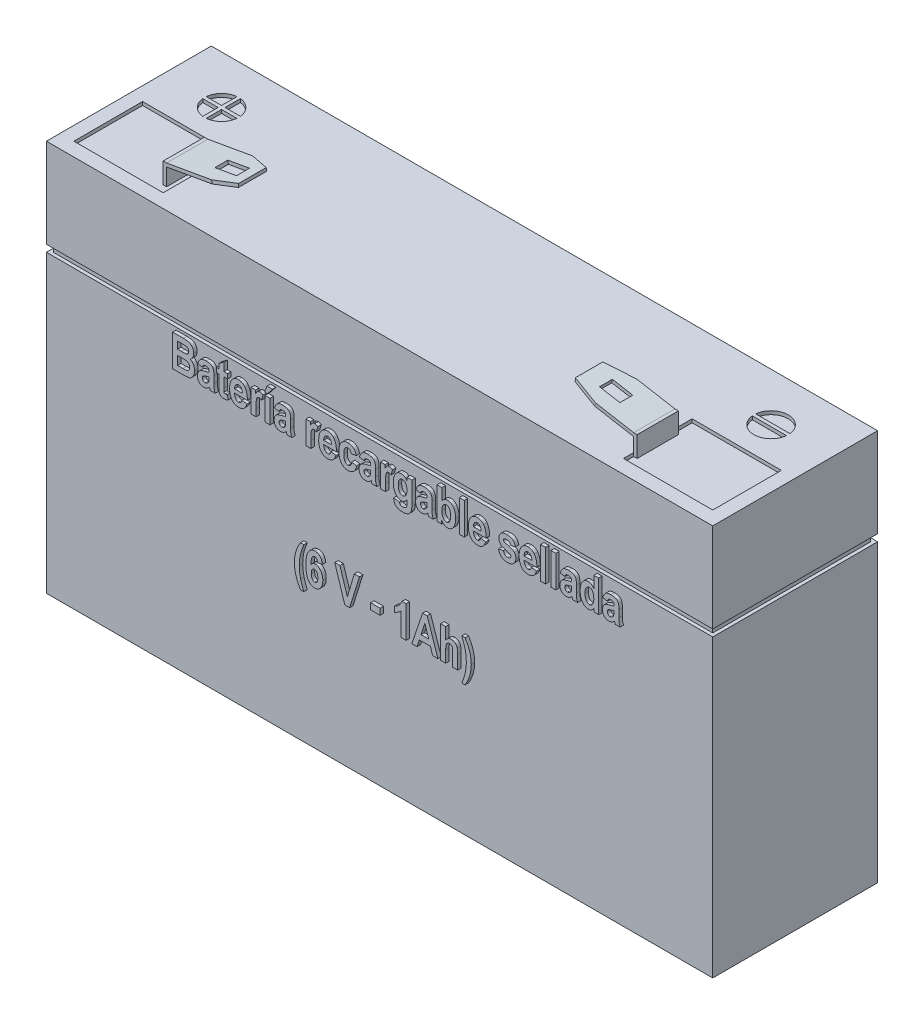
from build123d import *

# Parameters (mm, degrees)
CROQUIS1_W                = 97
CROQUIS1_H                = 57
SALIENTE_EXTRUIR1_DEPTH   = 12
CORTAR_EXTRUIR1_REACH     = 103.81
CROQUIS2_W                = 1
CROQUIS2_H                = 1
CORTAR_EXTRUIR2_REACH     = 63.16
CROQUIS4_W                = 1
CROQUIS4_H                = 1
CROQUIS5_W                = 13
CROQUIS5_H                = 10
CORTAR_EXTRUIR3_DEPTH     = 0.5
SALIENTE_EXTRUIR2_DEPTH   = 6
SALIENTE_EXTRUIR2_2_DEPTH = 6
CROQUIS7_W                = 3.203911074
CROQUIS7_H                = 1.884900202
CORTAR_EXTRUIR4_DEPTH     = 0.492404
CROQUIS8_W                = 3.00697096
CROQUIS8_H                = 1.873866852
CORTAR_EXTRUIR5_DEPTH     = 0.492404
CROQUIS10_W               = 0.720463423
CROQUIS10_H               = 3.362162642
CROQUIS10_H_2             = 4.622973633
CROQUIS10_W_2             = 0.720463424
CROQUIS10_W_3             = 1.380888228
CROQUIS10_H_3             = 0.900579279
SALIENTE_EXTRUIR4_DEPTH   = 0.5


with BuildPart() as part:
    # Croquis1 → Saliente-Extruir1 (new, symmetric)
    with BuildSketch(Plane.XY):
        Rectangle(CROQUIS1_W, CROQUIS1_H)
    extrude(amount=SALIENTE_EXTRUIR1_DEPTH, both=True)

    # Croquis2 → Cortar-Extruir1 (cut, up to next)
    with BuildSketch(Plane(origin=(48.5, 0, 0), x_dir=(0, 0, -1), z_dir=(1, 0, 0)), mode=Mode.PRIVATE) as cortar_extruir1_sk1:
        with Locations((-12, 15)):
            Rectangle(CROQUIS2_W, CROQUIS2_H)
    cortar_extruir1_tool1 = extrude(cortar_extruir1_sk1.sketch, amount=-CORTAR_EXTRUIR1_REACH, mode=Mode.PRIVATE) & part.part
    cortar_extruir1 = cortar_extruir1_tool1.solids().sort_by_distance((48.5, 15, 12))[0]
    add(cortar_extruir1, mode=Mode.SUBTRACT)

    # Simetría2: Cortar-Extruir1 across plane
    add(cortar_extruir1.mirror(Plane.XY), mode=Mode.SUBTRACT)

    # Croquis4 → Cortar-Extruir2 (cut, up to next)
    with BuildSketch(Plane.XY.offset(12), mode=Mode.PRIVATE) as cortar_extruir2_sk1:
        with Locations((48.5, 15)):
            Rectangle(CROQUIS4_W, CROQUIS4_H)
    cortar_extruir2_tool1 = extrude(cortar_extruir2_sk1.sketch, amount=-CORTAR_EXTRUIR2_REACH, mode=Mode.PRIVATE) & part.part
    cortar_extruir2 = cortar_extruir2_tool1.solids().sort_by_distance((48.5, 15, 12))[0]
    add(cortar_extruir2, mode=Mode.SUBTRACT)

    # Simetría3: Cortar-Extruir2 across plane
    add(cortar_extruir2.mirror(Plane(origin=(0, 0, 0), x_dir=(0, 0, 1), z_dir=(1, 0, 0))), mode=Mode.SUBTRACT)

    # Croquis5 → Cortar-Extruir3 (cut)
    with BuildSketch(Plane(origin=(0, 28.5, 0), x_dir=(1, 0, 0), z_dir=(0, 1, 0))):
        with Locations((-40, -5)):
            Rectangle(CROQUIS5_W, CROQUIS5_H)
        with Locations((40, -5)):
            Rectangle(CROQUIS5_W, CROQUIS5_H)
        with BuildLine():
            Line((42.487468593, 4.75), (37.512531407, 4.75))
            ThreePointArc((37.512531407, 4.75), (40, 2.5), (42.487468593, 4.75))
        make_face()
        with BuildLine():
            ThreePointArc((42.487468593, 5.25), (40, 7.5), (37.512531407, 5.25))
            Line((37.512531407, 5.25), (42.487468593, 5.25))
        make_face()
        with BuildLine():
            ThreePointArc((-40.25, 7.487468593), (-41.767766953, 6.767766953), (-42.487468593, 5.25))
            Line((-42.487468593, 5.25), (-40.25, 5.25))
            Line((-40.25, 5.25), (-40.25, 7.487468593))
        make_face()
        with BuildLine():
            Line((-39.75, 7.487468593), (-39.75, 5.25))
            Line((-39.75, 5.25), (-37.512531407, 5.25))
            ThreePointArc((-37.512531407, 5.25), (-38.232233047, 6.767766953), (-39.75, 7.487468593))
        make_face()
        with BuildLine():
            Line((-40.25, 4.75), (-42.487468593, 4.75))
            ThreePointArc((-42.487468593, 4.75), (-41.767766953, 3.232233047), (-40.25, 2.512531407))
            Line((-40.25, 2.512531407), (-40.25, 4.75))
        make_face()
        with BuildLine():
            Line((-37.512531407, 4.75), (-39.75, 4.75))
            Line((-39.75, 4.75), (-39.75, 2.512531407))
            ThreePointArc((-39.75, 2.512531407), (-38.232233047, 3.232233047), (-37.512531407, 4.75))
        make_face()
    extrude(amount=-CORTAR_EXTRUIR3_DEPTH, mode=Mode.SUBTRACT)

    # Croquis10 → Saliente-Extruir4 (add)
    # profile 1 of 33: a face of its own
    with BuildSketch(Plane.XY.offset(12)):
        with BuildLine():
            Line((-29.618842078, 14.122973633), (-28.065342822, 14.122973633))
            add(Edge.make_bspline(
                [(-28.065342822, 14.122973633), (-28.014371572, 14.122516168), (-27.916159233, 14.121634716), (-27.774698899, 14.117670552), (-27.645210416, 14.107968506), (-27.527600766, 14.095760345), (-27.421490266, 14.081827837), (-27.327439657, 14.061535065), (-27.244597163, 14.039992335), (-27.150159459, 14.00463133), (-27.043559009, 13.947853705), (-26.929037071, 13.857536608), (-26.823604313, 13.747436845), (-26.731790443, 13.617064327), (-26.653361906, 13.472522823), (-26.596871008, 13.315804161), (-26.563214485, 13.149090681), (-26.559016891, 13.034930545), (-26.556872529, 12.976611259)],
                knots=[0, 0, 0, 0, 1.124473672, 2.166656478, 3.121089245, 3.988001344, 4.77526076, 5.480116183, 6.109319004, 6.661554265, 7.701543192, 8.758483104, 9.865986798, 11.052779462, 12.265628083, 13.483214642, 14.714287386, 16, 16, 16, 16], degree=3))
            add(Edge.make_bspline(
                [(-26.556872529, 12.976611259), (-26.558785985, 12.923039389), (-26.562546937, 12.81774236), (-26.5889135, 12.663710132), (-26.634453061, 12.517842689), (-26.696978085, 12.381899573), (-26.773277427, 12.258036378), (-26.862170568, 12.150418855), (-26.960629245, 12.058036768), (-27.035699663, 12.011704333), (-27.072829408, 11.988788362)],
                knots=[0, 0, 0, 0, 1.102195328, 2.166396157, 3.204342149, 4.237991037, 5.237902837, 6.188656202, 7.104111395, 8, 8, 8, 8], degree=3))
            add(Edge.make_bspline(
                [(-27.072829408, 11.988788362), (-27.025049229, 11.966599797), (-26.9299294, 11.922427242), (-26.802600093, 11.827859236), (-26.694078339, 11.709874863), (-26.600750248, 11.57340171), (-26.526497899, 11.417811661), (-26.474483441, 11.244769279), (-26.441957166, 11.056285652), (-26.43855223, 10.925117864), (-26.436795292, 10.857435643)],
                knots=[0, 0, 0, 0, 0.914365049, 1.820299747, 2.735925076, 3.690630122, 4.685376883, 5.720815912, 6.823947219, 8, 8, 8, 8], degree=3))
            add(Edge.make_bspline(
                [(-26.436795292, 10.857435643), (-26.437514807, 10.81551314), (-26.438924328, 10.733387573), (-26.450026445, 10.61259047), (-26.470352352, 10.497164291), (-26.495640586, 10.386047522), (-26.531269415, 10.280801715), (-26.572032589, 10.179601127), (-26.622149593, 10.08378219), (-26.679233866, 9.993581443), (-26.74030499, 9.909549405), (-26.805788907, 9.83416509), (-26.872716714, 9.766140203), (-26.943949391, 9.707798224), (-27.017047185, 9.656737589), (-27.093201757, 9.614117696), (-27.172731921, 9.581027195), (-27.227448936, 9.565161315), (-27.25482147, 9.557224308)],
                knots=[0, 0, 0, 0, 1.22020471, 2.390363083, 3.526102761, 4.629955915, 5.703561803, 6.756598922, 7.802848293, 8.845806378, 9.861642828, 10.823224211, 11.750015592, 12.6357154, 13.499202288, 14.342595175, 15.170872714, 16, 16, 16, 16], degree=3))
            add(Edge.make_bspline(
                [(-27.25482147, 9.557224308), (-27.277296879, 9.552632458), (-27.328242933, 9.542223897), (-27.414654139, 9.530306405), (-27.519922416, 9.521923792), (-27.644015519, 9.512798597), (-27.787651742, 9.508221157), (-27.950238249, 9.503133465), (-28.131940188, 9.50050287), (-28.259217064, 9.500173286), (-28.326135571, 9.5)],
                knots=[0, 0, 0, 0, 0.512375785, 1.161426047, 1.946914314, 2.871141027, 3.940743941, 5.156722563, 6.50508681, 8, 8, 8, 8], degree=3))
            Line((-28.326135571, 9.5), (-29.618842078, 9.5))
            Line((-29.618842078, 9.5), (-29.618842078, 14.122973633))
        make_face()
        with BuildLine():
            Line((-28.898378655, 13.342471591), (-28.898378655, 12.321815075))
            Line((-28.898378655, 12.321815075), (-28.346773846, 12.321815075))
            add(Edge.make_bspline(
                [(-28.346773846, 12.321815075), (-28.307372878, 12.321709196), (-28.232322043, 12.321507518), (-28.125696008, 12.322858442), (-28.030932857, 12.323273062), (-27.948395291, 12.325593596), (-27.877688619, 12.326913063), (-27.818933124, 12.330138965), (-27.771625594, 12.332288141), (-27.744188811, 12.335454537), (-27.732316109, 12.336824729)],
                knots=[0, 0, 0, 0, 1.537921726, 2.929428249, 4.162267198, 5.236648627, 6.152403654, 6.922235861, 7.533619789, 8, 8, 8, 8], degree=3))
            add(Edge.make_bspline(
                [(-27.732316109, 12.336824729), (-27.698311813, 12.34303885), (-27.633130077, 12.354950497), (-27.541997913, 12.387976158), (-27.46345864, 12.434451064), (-27.395718349, 12.492292125), (-27.34319082, 12.563843687), (-27.303490415, 12.646242016), (-27.281232373, 12.740938702), (-27.278672471, 12.807638619), (-27.277335952, 12.84246247)],
                knots=[0, 0, 0, 0, 1.100193615, 2.108925541, 3.069258182, 3.994366649, 4.926956476, 5.876216083, 6.891177988, 8, 8, 8, 8], degree=3))
            add(Edge.make_bspline(
                [(-27.277335952, 12.84246247), (-27.278629093, 12.873819677), (-27.281096191, 12.933644004), (-27.2988869, 13.019156981), (-27.329927024, 13.095294318), (-27.373589335, 13.161047939), (-27.425255884, 13.216489804), (-27.482724256, 13.261309357), (-27.546070193, 13.293967916), (-27.605160944, 13.311591255), (-27.662317946, 13.321423739), (-27.72166701, 13.325896577), (-27.796940113, 13.332335536), (-27.888987259, 13.334918885), (-27.997447717, 13.339555442), (-28.12226009, 13.340384863), (-28.263272877, 13.343095984), (-28.36271967, 13.342687424), (-28.415255396, 13.342471591)],
                knots=[0, 0, 0, 0, 1.052351386, 2.007711197, 2.916182618, 3.795496935, 4.642249233, 5.450649971, 6.230038409, 7.020378978, 7.510527392, 8.174883014, 9.017067762, 10.046711282, 11.265182827, 12.661551488, 14.236365296, 16, 16, 16, 16], degree=3))
            Line((-28.415255396, 13.342471591), (-28.898378655, 13.342471591))
        make_face(mode=Mode.SUBTRACT)
        with BuildLine():
            Line((-28.898378655, 11.541313033), (-28.898378655, 10.280502042))
            Line((-28.898378655, 10.280502042), (-28.136638681, 10.280502042))
            add(Edge.make_bspline(
                [(-28.136638681, 10.280502042), (-28.096612944, 10.280761429), (-28.020309599, 10.281255914), (-27.911774614, 10.282786064), (-27.814502222, 10.286556299), (-27.728436141, 10.291823773), (-27.653420577, 10.299606845), (-27.589703082, 10.307238209), (-27.537489047, 10.317824263), (-27.482338216, 10.331996736), (-27.423232578, 10.359574409), (-27.359814267, 10.403022688), (-27.302506859, 10.459130589), (-27.251420203, 10.526064265), (-27.208455625, 10.604451865), (-27.17929413, 10.693844691), (-27.159528833, 10.792468536), (-27.158036241, 10.861706437), (-27.157258715, 10.897774089)],
                knots=[0, 0, 0, 0, 1.422074328, 2.710981391, 3.856134465, 4.880390511, 5.773592636, 6.5356346, 7.158764273, 7.665440749, 8.555459036, 9.45835037, 10.38545437, 11.392024878, 12.440928025, 13.544085548, 14.72065637, 16, 16, 16, 16], degree=3))
            add(Edge.make_bspline(
                [(-27.157258715, 10.897774089), (-27.158524187, 10.934744832), (-27.160954989, 11.005760641), (-27.179301286, 11.107579039), (-27.212521388, 11.198659587), (-27.25787827, 11.27951305), (-27.314290127, 11.348696606), (-27.379173954, 11.407449336), (-27.453142926, 11.453757589), (-27.522638676, 11.482298131), (-27.586695323, 11.499888573), (-27.646474638, 11.51011631), (-27.717026822, 11.521140973), (-27.798882603, 11.527511051), (-27.89168338, 11.534874235), (-27.995918307, 11.537613697), (-28.111288628, 11.540963906), (-28.191983046, 11.541193114), (-28.234201436, 11.541313033)],
                knots=[0, 0, 0, 0, 1.220775758, 2.344945564, 3.400211975, 4.408337778, 5.392209119, 6.335627291, 7.286926182, 8.259293687, 8.805475582, 9.477947255, 10.260788822, 11.163063353, 12.188028698, 13.335114355, 14.605762531, 16, 16, 16, 16], degree=3))
            Line((-28.234201436, 11.541313033), (-28.898378655, 11.541313033))
        make_face(mode=Mode.SUBTRACT)
    # profile 2 of 33: a face of its own
    with BuildSketch(Plane.XY.offset(12)):
        with BuildLine():
            Line((-25.296061538, 11.841506126), (-25.956486343, 11.961583363))
            add(Edge.make_bspline(
                [(-25.956486343, 11.961583363), (-25.945940946, 12.002968946), (-25.925504933, 12.083170408), (-25.889200245, 12.19816255), (-25.846999787, 12.303925595), (-25.79878432, 12.400360496), (-25.74797418, 12.48894948), (-25.691047046, 12.56785092), (-25.628869157, 12.63735066), (-25.561930088, 12.699515167), (-25.487587248, 12.751986133), (-25.407335558, 12.798847955), (-25.318936419, 12.836761633), (-25.223118629, 12.867913135), (-25.120112353, 12.891804925), (-25.009539951, 12.909923258), (-24.891609568, 12.91988144), (-24.810454062, 12.921415025), (-24.768847419, 12.922201261)],
                knots=[0, 0, 0, 0, 1.213161704, 2.35099604, 3.423270074, 4.444309064, 5.411810394, 6.321635592, 7.202505659, 8.057645353, 8.910659784, 9.78225301, 10.693291771, 11.637217641, 12.641344003, 13.694345722, 14.817941737, 16, 16, 16, 16], degree=3))
            add(Edge.make_bspline(
                [(-24.768847419, 12.922201261), (-24.731621461, 12.921981278), (-24.659295901, 12.921553878), (-24.554530057, 12.914267839), (-24.456132621, 12.905556852), (-24.364598289, 12.89170176), (-24.280030843, 12.872969646), (-24.202373328, 12.850229644), (-24.131246199, 12.824529284), (-24.046958072, 12.784747124), (-23.953825079, 12.726129832), (-23.856116205, 12.644400759), (-23.777615472, 12.54888933), (-23.724866061, 12.459727997), (-23.692493318, 12.377927667), (-23.671452875, 12.305038195), (-23.653631717, 12.220704524), (-23.640200418, 12.125052951), (-23.629073396, 12.018035115), (-23.620556575, 11.899786691), (-23.616229638, 11.770242641), (-23.615408025, 11.680155042), (-23.614980217, 11.633247167)],
                knots=[0, 0, 0, 0, 1.09282491, 2.123227397, 3.082570726, 3.992896761, 4.839445095, 5.623964566, 6.36765846, 7.057722888, 8.357080092, 9.58806459, 10.781349817, 11.970388213, 12.613201208, 13.35989331, 14.195515395, 15.142163347, 16.194706667, 17.354599644, 18.622561695, 20, 20, 20, 20], degree=3))
            Line((-23.614980217, 11.633247167), (-23.621546941, 10.599457203))
            add(Edge.make_bspline(
                [(-23.621546941, 10.599457203), (-23.621013605, 10.531594106), (-23.620020289, 10.405202007), (-23.612773178, 10.229336533), (-23.601141804, 10.081258057), (-23.584738078, 9.955294909), (-23.558040307, 9.842307003), (-23.526752665, 9.730427636), (-23.48489601, 9.615698349), (-23.451831248, 9.539235979), (-23.434864361, 9.5)],
                knots=[0, 0, 0, 0, 1.446763293, 2.694534366, 3.751396685, 4.613101426, 5.399095497, 6.224150885, 7.088738967, 8, 8, 8, 8], degree=3))
            Line((-23.434864361, 9.5), (-24.155327785, 9.5))
            Line((-24.155327785, 9.5), (-24.25007623, 9.867736539))
            add(Edge.make_bspline(
                [(-24.25007623, 9.867736539), (-24.28090584, 9.832297624), (-24.340686555, 9.763579155), (-24.440548303, 9.675100013), (-24.542616767, 9.600283143), (-24.648543121, 9.540671599), (-24.757518849, 9.495096057), (-24.869920185, 9.463072732), (-24.985831976, 9.443937431), (-25.064279604, 9.441292282), (-25.103750338, 9.439961381)],
                knots=[0, 0, 0, 0, 1.13982231, 2.210193057, 3.232630485, 4.208623403, 5.155090283, 6.095074437, 7.041541316, 8, 8, 8, 8], degree=3))
            add(Edge.make_bspline(
                [(-25.103750338, 9.439961381), (-25.136303788, 9.441007367), (-25.200385605, 9.443066401), (-25.294468997, 9.454992685), (-25.383822725, 9.476461961), (-25.46820126, 9.507491589), (-25.54924969, 9.544044942), (-25.624654869, 9.591820967), (-25.695402682, 9.647754926), (-25.761916078, 9.711058926), (-25.821402015, 9.78202413), (-25.873865518, 9.858888086), (-25.917477964, 9.941591004), (-25.954833826, 10.029507691), (-25.982594795, 10.123363918), (-26.00210432, 10.222943), (-26.014716652, 10.327708071), (-26.015914691, 10.399604053), (-26.016524962, 10.436227209)],
                knots=[0, 0, 0, 0, 1.028735983, 2.025077855, 2.990821541, 3.925278776, 4.862396134, 5.794499898, 6.737329222, 7.708666794, 8.690351064, 9.65771072, 10.643414134, 11.639804994, 12.671336525, 13.729311091, 14.843331846, 16, 16, 16, 16], degree=3))
            add(Edge.make_bspline(
                [(-26.016524962, 10.436227209), (-26.015258769, 10.482570957), (-26.012800936, 10.572529819), (-25.993978087, 10.702857106), (-25.962307141, 10.823917906), (-25.917039842, 10.935491805), (-25.859677447, 11.03656536), (-25.792676643, 11.128334874), (-25.713966934, 11.20795875), (-25.623847439, 11.280763316), (-25.512261366, 11.343886472), (-25.375578466, 11.400146845), (-25.212375642, 11.45640797), (-25.09278539, 11.486036188), (-25.028702065, 11.501912689)],
                knots=[0, 0, 0, 0, 1.038687772, 2.016219555, 2.944657485, 3.837696803, 4.707231328, 5.544282782, 6.377125776, 7.210293253, 8.133742114, 9.239263737, 10.520638948, 12, 12, 12, 12], degree=3))
            add(Edge.make_bspline(
                [(-25.028702065, 11.501912689), (-24.988952229, 11.511458231), (-24.9121054, 11.52991226), (-24.802063091, 11.558872716), (-24.701139572, 11.58733024), (-24.609526052, 11.613904361), (-24.527506552, 11.641065162), (-24.455193118, 11.668664462), (-24.39158307, 11.694048943), (-24.353175804, 11.712780677), (-24.335443641, 11.721428888)],
                knots=[0, 0, 0, 0, 1.346580109, 2.603291591, 3.747953046, 4.800679135, 5.74530354, 6.592834356, 7.350328893, 8, 8, 8, 8], degree=3))
            add(Edge.make_bspline(
                [(-24.335443641, 11.721428888), (-24.336158711, 11.762069385), (-24.337457954, 11.835910855), (-24.342186617, 11.935585285), (-24.35532657, 12.012088676), (-24.371222113, 12.070138828), (-24.397819203, 12.113198935), (-24.429665854, 12.149829762), (-24.470356807, 12.182422249), (-24.519501107, 12.210193914), (-24.577801924, 12.234336408), (-24.646744915, 12.25067191), (-24.726405207, 12.259441063), (-24.782896399, 12.260965673), (-24.812938279, 12.261776456)],
                knots=[0, 0, 0, 0, 1.705902181, 3.099527231, 4.177907969, 4.962080582, 5.603294938, 6.282059794, 6.990962425, 7.778529503, 8.643377977, 9.629736167, 10.73949939, 12, 12, 12, 12], degree=3))
            add(Edge.make_bspline(
                [(-24.812938279, 12.261776456), (-24.843361292, 12.260815288), (-24.901595668, 12.258975464), (-24.983569451, 12.241934624), (-25.056204611, 12.214876525), (-25.119317757, 12.174366003), (-25.174209493, 12.117608884), (-25.221606752, 12.04278281), (-25.263463397, 11.949081796), (-25.284696953, 11.879009888), (-25.296061538, 11.841506126)],
                knots=[0, 0, 0, 0, 1.03539786, 1.981912496, 2.838603353, 3.663089644, 4.514397679, 5.507264947, 6.665842792, 8, 8, 8, 8], degree=3))
        make_face()
        with BuildLine():
            add(Edge.make_bspline(
                [(-24.335443641, 11.121042702), (-24.361332502, 11.11147435), (-24.418948282, 11.090179939), (-24.515680079, 11.059616355), (-24.631555263, 11.026960361), (-24.715331505, 11.005179237), (-24.760404488, 10.993460638)],
                knots=[0, 0, 0, 0, 0.745990465, 1.660205234, 2.741152286, 4, 4, 4, 4], degree=3))
            add(Edge.make_bspline(
                [(-24.760404488, 10.993460638), (-24.81102473, 10.979565418), (-24.90385795, 10.954082766), (-25.026778796, 10.908258621), (-25.124144595, 10.863005476), (-25.17250261, 10.822672029), (-25.193808266, 10.804901851)],
                knots=[0, 0, 0, 0, 1.319989335, 2.42074818, 3.304210562, 4, 4, 4, 4], degree=3))
            add(Edge.make_bspline(
                [(-25.193808266, 10.804901851), (-25.209698969, 10.787081067), (-25.241286915, 10.751656456), (-25.273420779, 10.686494071), (-25.292335158, 10.614291676), (-25.294795564, 10.563616645), (-25.296061538, 10.537542378)],
                knots=[0, 0, 0, 0, 0.971770813, 1.931710932, 2.935785144, 4, 4, 4, 4], degree=3))
            add(Edge.make_bspline(
                [(-25.296061538, 10.537542378), (-25.294589632, 10.50770925), (-25.291747206, 10.450097939), (-25.270475606, 10.36686835), (-25.234600596, 10.291485087), (-25.185581302, 10.224730661), (-25.126468564, 10.168774792), (-25.056526956, 10.130057261), (-24.980509734, 10.103860177), (-24.926672348, 10.101558714), (-24.899243793, 10.100386186)],
                knots=[0, 0, 0, 0, 1.086352497, 2.097875641, 3.107085554, 4.109906568, 5.101791651, 6.045924234, 7.004456259, 8, 8, 8, 8], degree=3))
            add(Edge.make_bspline(
                [(-24.899243793, 10.100386186), (-24.873805137, 10.101735608), (-24.822564807, 10.104453709), (-24.746173376, 10.124256394), (-24.670943672, 10.156687292), (-24.597790219, 10.20029689), (-24.530815562, 10.253040093), (-24.471524801, 10.310439909), (-24.426361719, 10.374990096), (-24.395542739, 10.432215299), (-24.378530813, 10.484305982), (-24.366028365, 10.529857212), (-24.357512646, 10.58308526), (-24.348433108, 10.642692095), (-24.343691926, 10.709813286), (-24.338599601, 10.783885375), (-24.335967894, 10.865235194), (-24.335622809, 10.921850933), (-24.335443641, 10.951245984)],
                knots=[0, 0, 0, 0, 1.054768422, 2.124588751, 3.252311559, 4.444883932, 5.646454856, 6.783985427, 7.853254971, 8.903465755, 9.465533322, 10.123225916, 10.861233196, 11.699705318, 12.624105391, 13.651060796, 14.780424146, 16, 16, 16, 16], degree=3))
            Line((-24.335443641, 10.951245984), (-24.335443641, 11.121042702))
        make_face(mode=Mode.SUBTRACT)
    # profile 3 of 33: a face of its own
    with BuildSketch(Plane.XY.offset(12)):
        with BuildLine():
            Line((-21.633705803, 12.862162642), (-21.633705803, 12.201737837))
            Line((-21.633705803, 12.201737837), (-22.174053371, 12.201737837))
            Line((-22.174053371, 12.201737837), (-22.174053371, 10.812406679))
            add(Edge.make_bspline(
                [(-22.174053371, 10.812406679), (-22.174261951, 10.776756268), (-22.174655361, 10.709514651), (-22.172063928, 10.614471115), (-22.170863738, 10.531256608), (-22.167437936, 10.460006525), (-22.165695305, 10.400448042), (-22.160285667, 10.353039664), (-22.156805381, 10.317060959), (-22.15170885, 10.297668721), (-22.149662682, 10.289883076)],
                knots=[0, 0, 0, 0, 1.633077519, 3.08021054, 4.355478899, 5.44504512, 6.34855798, 7.082647984, 7.631699186, 8, 8, 8, 8], degree=3))
            add(Edge.make_bspline(
                [(-22.149662682, 10.289883076), (-22.140930318, 10.270276813), (-22.124111754, 10.23251508), (-22.077855071, 10.190182984), (-22.019455471, 10.164535929), (-21.976398045, 10.161848044), (-21.953599068, 10.160424805)],
                knots=[0, 0, 0, 0, 1.014912622, 1.954725382, 2.917023759, 4, 4, 4, 4], degree=3))
            add(Edge.make_bspline(
                [(-21.953599068, 10.160424805), (-21.93320669, 10.161803533), (-21.887875023, 10.164868405), (-21.814639423, 10.182111289), (-21.72973366, 10.210099365), (-21.669851496, 10.233871029), (-21.637458217, 10.246730319)],
                knots=[0, 0, 0, 0, 0.743696261, 1.653215291, 2.730505911, 4, 4, 4, 4], degree=3))
            Line((-21.637458217, 10.246730319), (-21.573667185, 9.573172066))
            add(Edge.make_bspline(
                [(-21.573667185, 9.573172066), (-21.617902462, 9.55252355), (-21.707047975, 9.510911453), (-21.851431002, 9.471021955), (-22.003264836, 9.444405363), (-22.107639008, 9.441463264), (-22.160919923, 9.439961381)],
                knots=[0, 0, 0, 0, 0.962722774, 1.940135147, 2.948480444, 4, 4, 4, 4], degree=3))
            add(Edge.make_bspline(
                [(-22.160919923, 9.439961381), (-22.206413241, 9.441350828), (-22.293177517, 9.444000763), (-22.416109014, 9.470286088), (-22.526032055, 9.510460115), (-22.620559983, 9.571124183), (-22.700665721, 9.647378694), (-22.765699982, 9.73903854), (-22.817560225, 9.844821303), (-22.838587807, 9.92231483), (-22.84948783, 9.962484984)],
                knots=[0, 0, 0, 0, 1.15293289, 2.198858919, 3.176017355, 4.107271099, 5.027845833, 5.966073087, 6.945677641, 8, 8, 8, 8], degree=3))
            add(Edge.make_bspline(
                [(-22.84948783, 9.962484984), (-22.853096883, 9.979965392), (-22.861115007, 10.018801091), (-22.870163209, 10.083317758), (-22.877287753, 10.160034005), (-22.884025615, 10.248524273), (-22.888197733, 10.349275626), (-22.892275773, 10.46152617), (-22.893748906, 10.586007966), (-22.894252387, 10.672942205), (-22.894516794, 10.718596337)],
                knots=[0, 0, 0, 0, 0.564600368, 1.254355734, 2.059595509, 3.00198767, 4.061704179, 5.249535203, 6.555573924, 8, 8, 8, 8], degree=3))
            Line((-22.894516794, 10.718596337), (-22.894516794, 12.201737837))
            Line((-22.894516794, 12.201737837), (-23.254748506, 12.201737837))
            Line((-23.254748506, 12.201737837), (-23.254748506, 12.862162642))
            Line((-23.254748506, 12.862162642), (-22.894516794, 12.862162642))
            Line((-22.894516794, 12.862162642), (-22.894516794, 13.537597101))
            Line((-22.894516794, 13.537597101), (-22.174053371, 14.062935014))
            Line((-22.174053371, 14.062935014), (-22.174053371, 12.862162642))
            Line((-22.174053371, 12.862162642), (-21.633705803, 12.862162642))
        make_face()
    # profile 4 of 33: a face of its own
    with BuildSketch(Plane.XY.offset(12)):
        with BuildLine():
            Line((-19.532354152, 10.580695135), (-18.811890729, 10.460617898))
            add(Edge.make_bspline(
                [(-18.811890729, 10.460617898), (-18.824144715, 10.418531081), (-18.848076587, 10.33633609), (-18.892622234, 10.219059551), (-18.941251555, 10.109928566), (-18.994574871, 10.008934605), (-19.053782065, 9.916805257), (-19.118050996, 9.832989629), (-19.185974828, 9.75618486), (-19.261007346, 9.689992784), (-19.338772603, 9.630030715), (-19.422073627, 9.579376031), (-19.508982514, 9.536267069), (-19.600353681, 9.501041515), (-19.695609516, 9.474279069), (-19.79500435, 9.454475701), (-19.898509408, 9.441761503), (-19.969159827, 9.440568998), (-20.005158273, 9.439961381)],
                knots=[0, 0, 0, 0, 1.232714057, 2.407474081, 3.525740945, 4.592223854, 5.617079511, 6.602360518, 7.561574953, 8.495942672, 9.412584555, 10.320830318, 11.233538188, 12.138583263, 13.071417567, 14.013373849, 14.987756094, 16, 16, 16, 16], degree=3))
            add(Edge.make_bspline(
                [(-20.005158273, 9.439961381), (-20.054310117, 9.441246629), (-20.150170931, 9.443753247), (-20.289819902, 9.462556079), (-20.420878236, 9.49453145), (-20.54342503, 9.538470592), (-20.657350553, 9.595125997), (-20.762145953, 9.665228119), (-20.858757835, 9.747984021), (-20.91491613, 9.811981576), (-20.943261689, 9.844283954)],
                knots=[0, 0, 0, 0, 1.115161021, 2.174897944, 3.190304242, 4.171206351, 5.123219486, 6.069849103, 7.025768057, 8, 8, 8, 8], degree=3))
            add(Edge.make_bspline(
                [(-20.943261689, 9.844283954), (-20.974446339, 9.884962849), (-21.037464359, 9.967166865), (-21.11740231, 10.103293676), (-21.183401737, 10.251614977), (-21.239563154, 10.410723627), (-21.280763444, 10.582529076), (-21.312061972, 10.765475219), (-21.329433497, 10.960293453), (-21.332129314, 11.093805606), (-21.33351271, 11.162319253)],
                knots=[0, 0, 0, 0, 0.876816242, 1.771872474, 2.694187044, 3.652337651, 4.655867876, 5.714487856, 6.827157152, 8, 8, 8, 8], degree=3))
            add(Edge.make_bspline(
                [(-21.33351271, 11.162319253), (-21.332154298, 11.230213324), (-21.329507764, 11.362488362), (-21.311745216, 11.555975749), (-21.28124435, 11.739268348), (-21.236875587, 11.911931207), (-21.181764247, 12.074893177), (-21.113176976, 12.226848073), (-21.032495656, 12.36919631), (-20.968539545, 12.455930526), (-20.936694965, 12.49911662)],
                knots=[0, 0, 0, 0, 1.146796484, 2.234253234, 3.278893813, 4.281992692, 5.242465425, 6.181018207, 7.094305297, 8, 8, 8, 8], degree=3))
            add(Edge.make_bspline(
                [(-20.936694965, 12.49911662), (-20.908414872, 12.533024264), (-20.853019254, 12.599443241), (-20.757615289, 12.684568572), (-20.65839001, 12.759184379), (-20.55112288, 12.817897326), (-20.439009264, 12.865987525), (-20.319923448, 12.898174256), (-20.195055597, 12.91868287), (-20.10968387, 12.921012762), (-20.066134995, 12.922201261)],
                knots=[0, 0, 0, 0, 1.054423228, 2.065425522, 3.04949579, 4.016891036, 4.982058557, 5.959887573, 6.959320554, 8, 8, 8, 8], degree=3))
            add(Edge.make_bspline(
                [(-20.066134995, 12.922201261), (-20.017887979, 12.921134744), (-19.92374107, 12.919053594), (-19.786869121, 12.897146026), (-19.657462109, 12.865302566), (-19.536195153, 12.817762673), (-19.423130234, 12.756554745), (-19.31835063, 12.68178595), (-19.221507055, 12.593981065), (-19.165113125, 12.5267115), (-19.13647451, 12.492549896)],
                knots=[0, 0, 0, 0, 1.088682434, 2.124402561, 3.12298092, 4.093444635, 5.057230266, 6.019384489, 6.994181053, 8, 8, 8, 8], degree=3))
            add(Edge.make_bspline(
                [(-19.13647451, 12.492549896), (-19.105080923, 12.449772151), (-19.041034522, 12.362500803), (-18.963182948, 12.215572057), (-18.896696219, 12.055215147), (-18.840786763, 11.880635709), (-18.799462995, 11.690805004), (-18.770136228, 11.486691263), (-18.750517339, 11.268393196), (-18.748922393, 11.117961014), (-18.748099696, 11.040365809)],
                knots=[0, 0, 0, 0, 0.831163965, 1.695666726, 2.599069064, 3.551260179, 4.566077474, 5.641675786, 6.783540543, 8, 8, 8, 8], degree=3))
            Line((-18.748099696, 11.040365809), (-18.75185211, 10.940926847))
            Line((-18.75185211, 10.940926847), (-20.613049287, 10.940926847))
            add(Edge.make_bspline(
                [(-20.613049287, 10.940926847), (-20.611828399, 10.90838693), (-20.609452418, 10.845060737), (-20.600294658, 10.752866203), (-20.585248902, 10.666719837), (-20.565635373, 10.58601601), (-20.54048271, 10.510881792), (-20.509596818, 10.441507326), (-20.473550282, 10.37766252), (-20.432543234, 10.319942287), (-20.387802445, 10.268480311), (-20.340068315, 10.22392742), (-20.29117309, 10.185009361), (-20.238201984, 10.15501039), (-20.18418683, 10.130067831), (-20.127244018, 10.113465129), (-20.068423392, 10.102610809), (-20.028347568, 10.101135997), (-20.007972584, 10.100386186)],
                knots=[0, 0, 0, 0, 1.35591678, 2.638760514, 3.854825, 4.995029552, 6.094573698, 7.149727403, 8.152807325, 9.142869075, 10.093520324, 10.987160547, 11.859773256, 12.688425387, 13.516156053, 14.33191691, 15.15192844, 16, 16, 16, 16], degree=3))
            add(Edge.make_bspline(
                [(-20.007972584, 10.100386186), (-19.979358512, 10.101727394), (-19.923681102, 10.104337124), (-19.844036271, 10.127678018), (-19.772116735, 10.166238651), (-19.707344796, 10.219504856), (-19.651838185, 10.2891724), (-19.602778981, 10.372335358), (-19.562847808, 10.471280079), (-19.542875473, 10.542943317), (-19.532354152, 10.580695135)],
                knots=[0, 0, 0, 0, 0.932193119, 1.813866296, 2.681250778, 3.580176035, 4.530074106, 5.573134138, 6.721539785, 8, 8, 8, 8], degree=3))
        make_face()
        with BuildLine():
            add(Edge.make_bspline(
                [(-19.472315533, 11.481274414), (-19.473544555, 11.512561873), (-19.475933928, 11.573388598), (-19.484956564, 11.661877713), (-19.500434988, 11.744089001), (-19.51831542, 11.82071548), (-19.543431084, 11.890740753), (-19.571960804, 11.955394122), (-19.605757434, 12.014058837), (-19.656379548, 12.08139358), (-19.726618573, 12.152295194), (-19.821528946, 12.216088151), (-19.92600426, 12.25498442), (-19.998587924, 12.259500091), (-20.035177583, 12.261776456)],
                knots=[0, 0, 0, 0, 1.052132604, 2.045477051, 2.985358942, 3.862085385, 4.686292675, 5.481173856, 6.234546503, 6.955412018, 8.307748233, 9.566804135, 10.773418122, 12, 12, 12, 12], degree=3))
            add(Edge.make_bspline(
                [(-20.035177583, 12.261776456), (-20.073665627, 12.259241479), (-20.149428127, 12.254251457), (-20.257929303, 12.21435358), (-20.357039782, 12.149510245), (-20.410151539, 12.08933438), (-20.437623948, 12.058208015)],
                knots=[0, 0, 0, 0, 0.987545932, 1.943952958, 2.936496012, 4, 4, 4, 4], degree=3))
            add(Edge.make_bspline(
                [(-20.437623948, 12.058208015), (-20.45079555, 12.040309801), (-20.47742288, 12.004127288), (-20.511447218, 11.94452996), (-20.539135415, 11.879439138), (-20.56301329, 11.809665139), (-20.580585176, 11.734534699), (-20.592345501, 11.654498124), (-20.600355183, 11.569619278), (-20.600684354, 11.511313549), (-20.600853942, 11.481274414)],
                knots=[0, 0, 0, 0, 0.872144774, 1.763102678, 2.686959297, 3.646047413, 4.655680246, 5.711519297, 6.820973795, 8, 8, 8, 8], degree=3))
            Line((-20.600853942, 11.481274414), (-19.472315533, 11.481274414))
        make_face(mode=Mode.SUBTRACT)
    # profile 5 of 33: a face of its own
    with BuildSketch(Plane.XY.offset(12)):
        with BuildLine():
            Line((-17.491041119, 9.5), (-18.211504542, 9.5))
            Line((-18.211504542, 9.5), (-18.211504542, 12.862162642))
            Line((-18.211504542, 12.862162642), (-17.551079738, 12.862162642))
            Line((-17.551079738, 12.862162642), (-17.551079738, 12.384668003))
            add(Edge.make_bspline(
                [(-17.551079738, 12.384668003), (-17.537087023, 12.411290417), (-17.510135955, 12.462567278), (-17.470044058, 12.535754278), (-17.431033375, 12.601971362), (-17.391211795, 12.659280619), (-17.355150916, 12.711124389), (-17.318151949, 12.754203038), (-17.282983902, 12.790824244), (-17.238150515, 12.82979504), (-17.178848209, 12.866711454), (-17.103063244, 12.899315013), (-17.021345965, 12.918321077), (-16.965173425, 12.920893664), (-16.936622, 12.922201261)],
                knots=[0, 0, 0, 0, 1.247976544, 2.403700946, 3.462962112, 4.43467857, 5.299009931, 6.081551121, 6.788109263, 7.404564201, 8.542080144, 9.670008541, 10.815710014, 12, 12, 12, 12], degree=3))
            add(Edge.make_bspline(
                [(-16.936622, 12.922201261), (-16.896048889, 12.920343552), (-16.814879677, 12.916627083), (-16.695645111, 12.882065338), (-16.578729356, 12.829772627), (-16.507182944, 12.779920901), (-16.470384603, 12.754280749)],
                knots=[0, 0, 0, 0, 0.96387831, 1.928302751, 2.934467569, 4, 4, 4, 4], degree=3))
            Line((-16.470384603, 12.754280749), (-16.698343733, 11.996293189))
            add(Edge.make_bspline(
                [(-16.698343733, 11.996293189), (-16.726160875, 12.018512499), (-16.778738845, 12.060509846), (-16.863278888, 12.105687295), (-16.945270557, 12.135646745), (-17.000187033, 12.139729574), (-17.026679928, 12.141699219)],
                knots=[0, 0, 0, 0, 1.164920977, 2.201850213, 3.13253367, 4, 4, 4, 4], degree=3))
            add(Edge.make_bspline(
                [(-17.026679928, 12.141699219), (-17.050319328, 12.140629567), (-17.097380481, 12.138500111), (-17.164845121, 12.115273915), (-17.22837593, 12.08010923), (-17.286817459, 12.028699603), (-17.340007334, 11.959134162), (-17.381864287, 11.86615436), (-17.418051798, 11.752290061), (-17.440421854, 11.64075166), (-17.454493963, 11.535530676), (-17.464912823, 11.438587439), (-17.473063644, 11.326259063), (-17.479229413, 11.198623972), (-17.485112385, 11.055728788), (-17.488678266, 10.897165265), (-17.490295703, 10.722977625), (-17.490785912, 10.601646393), (-17.491041119, 10.538480481)],
                knots=[0, 0, 0, 0, 0.622595437, 1.239458642, 1.864845878, 2.532755744, 3.28162568, 4.161487658, 5.21226045, 6.436118557, 7.162012101, 8.018184314, 9.012812002, 10.138387645, 11.395699311, 12.792934727, 14.330378767, 16, 16, 16, 16], degree=3))
            Line((-17.491041119, 10.538480481), (-17.491041119, 9.5))
        make_face()
    # profile 6 of 33: a face of its own
    with BuildSketch(Plane.XY.offset(12)):
        with Locations((-15.809959799, 11.181081321)):
            Rectangle(CROQUIS10_W, CROQUIS10_H)
    # profile 7 of 33: a face of its own
    with BuildSketch(Plane.XY.offset(12)):
        Polygon((-16.230230128, 13.282432972), (-15.884069968, 14.183012251), (-15.089496375, 14.183012251), (-15.782754799, 13.282432972), align=None)
    # profile 8 of 33: a face of its own
    with BuildSketch(Plane.XY.offset(12)):
        with BuildLine():
            Line((-14.128878477, 11.841506126), (-14.789303282, 11.961583363))
            add(Edge.make_bspline(
                [(-14.789303282, 11.961583363), (-14.778757884, 12.002968946), (-14.758321872, 12.083170408), (-14.722017184, 12.19816255), (-14.679816726, 12.303925595), (-14.631601259, 12.400360496), (-14.580791119, 12.48894948), (-14.523863985, 12.56785092), (-14.461686096, 12.63735066), (-14.394747027, 12.699515167), (-14.320404187, 12.751986133), (-14.240152497, 12.798847955), (-14.151753358, 12.836761633), (-14.055935568, 12.867913135), (-13.952929291, 12.891804925), (-13.84235689, 12.909923258), (-13.724426507, 12.91988144), (-13.643271001, 12.921415025), (-13.601664358, 12.922201261)],
                knots=[0, 0, 0, 0, 1.213161704, 2.35099604, 3.423270074, 4.444309064, 5.411810394, 6.321635592, 7.202505659, 8.057645353, 8.910659784, 9.78225301, 10.693291771, 11.637217641, 12.641344003, 13.694345722, 14.817941737, 16, 16, 16, 16], degree=3))
            add(Edge.make_bspline(
                [(-13.601664358, 12.922201261), (-13.5644384, 12.921981278), (-13.49211284, 12.921553878), (-13.387346996, 12.914267839), (-13.28894956, 12.905556852), (-13.197415228, 12.89170176), (-13.112847782, 12.872969646), (-13.035190266, 12.850229644), (-12.964063138, 12.824529284), (-12.879775011, 12.784747124), (-12.786642018, 12.726129832), (-12.688933144, 12.644400759), (-12.610432411, 12.54888933), (-12.557683, 12.459727997), (-12.525310256, 12.377927667), (-12.504269814, 12.305038195), (-12.486448656, 12.220704524), (-12.473017357, 12.125052951), (-12.461890335, 12.018035115), (-12.453373514, 11.899786691), (-12.449046577, 11.770242641), (-12.448224964, 11.680155042), (-12.447797156, 11.633247167)],
                knots=[0, 0, 0, 0, 1.09282491, 2.123227397, 3.082570726, 3.992896761, 4.839445095, 5.623964566, 6.36765846, 7.057722888, 8.357080092, 9.58806459, 10.781349817, 11.970388213, 12.613201208, 13.35989331, 14.195515395, 15.142163347, 16.194706667, 17.354599644, 18.622561695, 20, 20, 20, 20], degree=3))
            Line((-12.447797156, 11.633247167), (-12.45436388, 10.599457203))
            add(Edge.make_bspline(
                [(-12.45436388, 10.599457203), (-12.453830544, 10.531594106), (-12.452837228, 10.405202007), (-12.445590117, 10.229336533), (-12.433958743, 10.081258057), (-12.417555017, 9.955294909), (-12.390857246, 9.842307003), (-12.359569604, 9.730427636), (-12.317712949, 9.615698349), (-12.284648187, 9.539235979), (-12.2676813, 9.5)],
                knots=[0, 0, 0, 0, 1.446763293, 2.694534366, 3.751396685, 4.613101426, 5.399095497, 6.224150885, 7.088738967, 8, 8, 8, 8], degree=3))
            Line((-12.2676813, 9.5), (-12.988144724, 9.5))
            Line((-12.988144724, 9.5), (-13.082893169, 9.867736539))
            add(Edge.make_bspline(
                [(-13.082893169, 9.867736539), (-13.113722779, 9.832297624), (-13.173503493, 9.763579155), (-13.273365242, 9.675100013), (-13.375433706, 9.600283143), (-13.48136006, 9.540671599), (-13.590335788, 9.495096057), (-13.702737124, 9.463072732), (-13.818648915, 9.443937431), (-13.897096543, 9.441292282), (-13.936567277, 9.439961381)],
                knots=[0, 0, 0, 0, 1.13982231, 2.210193057, 3.232630485, 4.208623403, 5.155090283, 6.095074437, 7.041541316, 8, 8, 8, 8], degree=3))
            add(Edge.make_bspline(
                [(-13.936567277, 9.439961381), (-13.969120727, 9.441007367), (-14.033202544, 9.443066401), (-14.127285936, 9.454992685), (-14.216639664, 9.476461961), (-14.301018199, 9.507491589), (-14.382066628, 9.544044942), (-14.457471808, 9.591820967), (-14.528219621, 9.647754926), (-14.594733016, 9.711058926), (-14.654218954, 9.78202413), (-14.706682457, 9.858888086), (-14.750294902, 9.941591004), (-14.787650765, 10.029507691), (-14.815411734, 10.123363918), (-14.834921259, 10.222943), (-14.847533591, 10.327708071), (-14.84873163, 10.399604053), (-14.8493419, 10.436227209)],
                knots=[0, 0, 0, 0, 1.028735983, 2.025077855, 2.990821541, 3.925278776, 4.862396134, 5.794499898, 6.737329222, 7.708666794, 8.690351064, 9.65771072, 10.643414134, 11.639804994, 12.671336525, 13.729311091, 14.843331846, 16, 16, 16, 16], degree=3))
            add(Edge.make_bspline(
                [(-14.8493419, 10.436227209), (-14.848075708, 10.482570957), (-14.845617875, 10.572529819), (-14.826795026, 10.702857106), (-14.79512408, 10.823917906), (-14.749856781, 10.935491805), (-14.692494386, 11.03656536), (-14.625493582, 11.128334874), (-14.546783872, 11.20795875), (-14.456664378, 11.280763316), (-14.345078305, 11.343886472), (-14.208395405, 11.400146845), (-14.045192581, 11.45640797), (-13.925602329, 11.486036188), (-13.861519004, 11.501912689)],
                knots=[0, 0, 0, 0, 1.038687772, 2.016219555, 2.944657485, 3.837696803, 4.707231328, 5.544282782, 6.377125776, 7.210293253, 8.133742114, 9.239263737, 10.520638948, 12, 12, 12, 12], degree=3))
            add(Edge.make_bspline(
                [(-13.861519004, 11.501912689), (-13.821769168, 11.511458231), (-13.744922339, 11.52991226), (-13.63488003, 11.558872716), (-13.533956511, 11.58733024), (-13.44234299, 11.613904361), (-13.360323491, 11.641065162), (-13.288010057, 11.668664462), (-13.224400009, 11.694048943), (-13.185992743, 11.712780677), (-13.168260579, 11.721428888)],
                knots=[0, 0, 0, 0, 1.346580109, 2.603291591, 3.747953046, 4.800679135, 5.74530354, 6.592834356, 7.350328893, 8, 8, 8, 8], degree=3))
            add(Edge.make_bspline(
                [(-13.168260579, 11.721428888), (-13.16897565, 11.762069385), (-13.170274893, 11.835910855), (-13.175003556, 11.935585285), (-13.188143509, 12.012088676), (-13.204039052, 12.070138828), (-13.230636142, 12.113198935), (-13.262482793, 12.149829762), (-13.303173746, 12.182422249), (-13.352318046, 12.210193914), (-13.410618863, 12.234336408), (-13.479561853, 12.25067191), (-13.559222146, 12.259441063), (-13.615713338, 12.260965673), (-13.645755218, 12.261776456)],
                knots=[0, 0, 0, 0, 1.705902181, 3.099527231, 4.177907969, 4.962080582, 5.603294938, 6.282059794, 6.990962425, 7.778529503, 8.643377977, 9.629736167, 10.73949939, 12, 12, 12, 12], degree=3))
            add(Edge.make_bspline(
                [(-13.645755218, 12.261776456), (-13.67617823, 12.260815288), (-13.734412607, 12.258975464), (-13.81638639, 12.241934624), (-13.889021549, 12.214876525), (-13.952134696, 12.174366003), (-14.007026432, 12.117608884), (-14.05442369, 12.04278281), (-14.096280336, 11.949081796), (-14.117513891, 11.879009888), (-14.128878477, 11.841506126)],
                knots=[0, 0, 0, 0, 1.03539786, 1.981912496, 2.838603353, 3.663089644, 4.514397679, 5.507264947, 6.665842792, 8, 8, 8, 8], degree=3))
        make_face()
        with BuildLine():
            add(Edge.make_bspline(
                [(-13.168260579, 11.121042702), (-13.194149441, 11.11147435), (-13.251765221, 11.090179939), (-13.348497018, 11.059616355), (-13.464372202, 11.026960361), (-13.548148444, 11.005179237), (-13.593221427, 10.993460638)],
                knots=[0, 0, 0, 0, 0.745990465, 1.660205234, 2.741152286, 4, 4, 4, 4], degree=3))
            add(Edge.make_bspline(
                [(-13.593221427, 10.993460638), (-13.643841669, 10.979565418), (-13.736674889, 10.954082766), (-13.859595735, 10.908258621), (-13.956961534, 10.863005476), (-14.005319549, 10.822672029), (-14.026625205, 10.804901851)],
                knots=[0, 0, 0, 0, 1.319989335, 2.42074818, 3.304210562, 4, 4, 4, 4], degree=3))
            add(Edge.make_bspline(
                [(-14.026625205, 10.804901851), (-14.042515908, 10.787081067), (-14.074103854, 10.751656456), (-14.106237718, 10.686494071), (-14.125152097, 10.614291676), (-14.127612503, 10.563616645), (-14.128878477, 10.537542378)],
                knots=[0, 0, 0, 0, 0.971770813, 1.931710932, 2.935785144, 4, 4, 4, 4], degree=3))
            add(Edge.make_bspline(
                [(-14.128878477, 10.537542378), (-14.127406571, 10.50770925), (-14.124564145, 10.450097939), (-14.103292545, 10.36686835), (-14.067417535, 10.291485087), (-14.018398241, 10.224730661), (-13.959285503, 10.168774792), (-13.889343895, 10.130057261), (-13.813326673, 10.103860177), (-13.759489287, 10.101558714), (-13.732060732, 10.100386186)],
                knots=[0, 0, 0, 0, 1.086352497, 2.097875641, 3.107085554, 4.109906568, 5.101791651, 6.045924234, 7.004456259, 8, 8, 8, 8], degree=3))
            add(Edge.make_bspline(
                [(-13.732060732, 10.100386186), (-13.706622076, 10.101735608), (-13.655381746, 10.104453709), (-13.578990315, 10.124256394), (-13.503760611, 10.156687292), (-13.430607158, 10.20029689), (-13.363632501, 10.253040093), (-13.30434174, 10.310439909), (-13.259178657, 10.374990096), (-13.228359678, 10.432215299), (-13.211347752, 10.484305982), (-13.198845304, 10.529857212), (-13.190329585, 10.58308526), (-13.181250047, 10.642692095), (-13.176508865, 10.709813286), (-13.171416539, 10.783885375), (-13.168784833, 10.865235194), (-13.168439748, 10.921850933), (-13.168260579, 10.951245984)],
                knots=[0, 0, 0, 0, 1.054768422, 2.124588751, 3.252311559, 4.444883932, 5.646454856, 6.783985427, 7.853254971, 8.903465755, 9.465533322, 10.123225916, 10.861233196, 11.699705318, 12.624105391, 13.651060796, 14.780424146, 16, 16, 16, 16], degree=3))
            Line((-13.168260579, 10.951245984), (-13.168260579, 11.121042702))
        make_face(mode=Mode.SUBTRACT)
    # profile 9 of 33: a face of its own
    with BuildSketch(Plane.XY.offset(12)):
        with BuildLine():
            Line((-9.505904844, 9.5), (-10.226368268, 9.5))
            Line((-10.226368268, 9.5), (-10.226368268, 12.862162642))
            Line((-10.226368268, 12.862162642), (-9.565943463, 12.862162642))
            Line((-9.565943463, 12.862162642), (-9.565943463, 12.384668003))
            add(Edge.make_bspline(
                [(-9.565943463, 12.384668003), (-9.551950748, 12.411290417), (-9.52499968, 12.462567278), (-9.484907783, 12.535754278), (-9.445897101, 12.601971362), (-9.40607552, 12.659280619), (-9.370014641, 12.711124389), (-9.333015674, 12.754203038), (-9.297847627, 12.790824244), (-9.25301424, 12.82979504), (-9.193711934, 12.866711454), (-9.117926969, 12.899315013), (-9.03620969, 12.918321077), (-8.980037151, 12.920893664), (-8.951485726, 12.922201261)],
                knots=[0, 0, 0, 0, 1.247976544, 2.403700946, 3.462962112, 4.43467857, 5.299009931, 6.081551121, 6.788109263, 7.404564201, 8.542080144, 9.670008541, 10.815710014, 12, 12, 12, 12], degree=3))
            add(Edge.make_bspline(
                [(-8.951485726, 12.922201261), (-8.910912614, 12.920343552), (-8.829743402, 12.916627083), (-8.710508836, 12.882065338), (-8.593593082, 12.829772627), (-8.522046669, 12.779920901), (-8.485248328, 12.754280749)],
                knots=[0, 0, 0, 0, 0.96387831, 1.928302751, 2.934467569, 4, 4, 4, 4], degree=3))
            Line((-8.485248328, 12.754280749), (-8.713207458, 11.996293189))
            add(Edge.make_bspline(
                [(-8.713207458, 11.996293189), (-8.7410246, 12.018512499), (-8.79360257, 12.060509846), (-8.878142613, 12.105687295), (-8.960134283, 12.135646745), (-9.015050758, 12.139729574), (-9.041543654, 12.141699219)],
                knots=[0, 0, 0, 0, 1.164920977, 2.201850213, 3.13253367, 4, 4, 4, 4], degree=3))
            add(Edge.make_bspline(
                [(-9.041543654, 12.141699219), (-9.065183054, 12.140629567), (-9.112244206, 12.138500111), (-9.179708847, 12.115273915), (-9.243239655, 12.08010923), (-9.301681184, 12.028699603), (-9.354871059, 11.959134162), (-9.396728012, 11.86615436), (-9.432915523, 11.752290061), (-9.455285579, 11.64075166), (-9.469357688, 11.535530676), (-9.479776548, 11.438587439), (-9.487927369, 11.326259063), (-9.494093138, 11.198623972), (-9.49997611, 11.055728788), (-9.503541991, 10.897165265), (-9.505159428, 10.722977625), (-9.505649638, 10.601646393), (-9.505904844, 10.538480481)],
                knots=[0, 0, 0, 0, 0.622595437, 1.239458642, 1.864845878, 2.532755744, 3.28162568, 4.161487658, 5.21226045, 6.436118557, 7.162012101, 8.018184314, 9.012812002, 10.138387645, 11.395699311, 12.792934727, 14.330378767, 16, 16, 16, 16], degree=3))
            Line((-9.505904844, 10.538480481), (-9.505904844, 9.5))
        make_face()
    # profile 10 of 33: a face of its own
    with BuildSketch(Plane.XY.offset(12)):
        with BuildLine():
            Line((-6.564012533, 10.580695135), (-5.843549109, 10.460617898))
            add(Edge.make_bspline(
                [(-5.843549109, 10.460617898), (-5.855803096, 10.418531081), (-5.879734968, 10.33633609), (-5.924280614, 10.219059551), (-5.972909936, 10.109928566), (-6.026233251, 10.008934605), (-6.085440446, 9.916805257), (-6.149709376, 9.832989629), (-6.217633209, 9.75618486), (-6.292665727, 9.689992784), (-6.370430984, 9.630030715), (-6.453732008, 9.579376031), (-6.540640894, 9.536267069), (-6.632012061, 9.501041515), (-6.727267897, 9.474279069), (-6.826662731, 9.454475701), (-6.930167788, 9.441761503), (-7.000818207, 9.440568998), (-7.036816654, 9.439961381)],
                knots=[0, 0, 0, 0, 1.232714057, 2.407474081, 3.525740945, 4.592223854, 5.617079511, 6.602360518, 7.561574953, 8.495942672, 9.412584555, 10.320830318, 11.233538188, 12.138583263, 13.071417567, 14.013373849, 14.987756094, 16, 16, 16, 16], degree=3))
            add(Edge.make_bspline(
                [(-7.036816654, 9.439961381), (-7.085968498, 9.441246629), (-7.181829312, 9.443753247), (-7.321478283, 9.462556079), (-7.452536616, 9.49453145), (-7.575083411, 9.538470592), (-7.689008934, 9.595125997), (-7.793804334, 9.665228119), (-7.890416215, 9.747984021), (-7.946574511, 9.811981576), (-7.97492007, 9.844283954)],
                knots=[0, 0, 0, 0, 1.115161021, 2.174897944, 3.190304242, 4.171206351, 5.123219486, 6.069849103, 7.025768057, 8, 8, 8, 8], degree=3))
            add(Edge.make_bspline(
                [(-7.97492007, 9.844283954), (-8.00610472, 9.884962849), (-8.06912274, 9.967166865), (-8.149060691, 10.103293676), (-8.215060118, 10.251614977), (-8.271221535, 10.410723627), (-8.312421825, 10.582529076), (-8.343720353, 10.765475219), (-8.361091877, 10.960293453), (-8.363787694, 11.093805606), (-8.365171091, 11.162319253)],
                knots=[0, 0, 0, 0, 0.876816242, 1.771872474, 2.694187044, 3.652337651, 4.655867876, 5.714487856, 6.827157152, 8, 8, 8, 8], degree=3))
            add(Edge.make_bspline(
                [(-8.365171091, 11.162319253), (-8.363812679, 11.230213324), (-8.361166145, 11.362488362), (-8.343403597, 11.555975749), (-8.312902731, 11.739268348), (-8.268533968, 11.911931207), (-8.213422628, 12.074893177), (-8.144835356, 12.226848073), (-8.064154036, 12.36919631), (-8.000197926, 12.455930526), (-7.968353346, 12.49911662)],
                knots=[0, 0, 0, 0, 1.146796484, 2.234253234, 3.278893813, 4.281992692, 5.242465425, 6.181018207, 7.094305297, 8, 8, 8, 8], degree=3))
            add(Edge.make_bspline(
                [(-7.968353346, 12.49911662), (-7.940073253, 12.533024264), (-7.884677635, 12.599443241), (-7.789273669, 12.684568572), (-7.69004839, 12.759184379), (-7.58278126, 12.817897326), (-7.470667645, 12.865987525), (-7.351581829, 12.898174256), (-7.226713978, 12.91868287), (-7.141342251, 12.921012762), (-7.097793376, 12.922201261)],
                knots=[0, 0, 0, 0, 1.054423228, 2.065425522, 3.04949579, 4.016891036, 4.982058557, 5.959887573, 6.959320554, 8, 8, 8, 8], degree=3))
            add(Edge.make_bspline(
                [(-7.097793376, 12.922201261), (-7.04954636, 12.921134744), (-6.955399451, 12.919053594), (-6.818527502, 12.897146026), (-6.689120489, 12.865302566), (-6.567853534, 12.817762673), (-6.454788615, 12.756554745), (-6.350009011, 12.68178595), (-6.253165436, 12.593981065), (-6.196771505, 12.5267115), (-6.168132891, 12.492549896)],
                knots=[0, 0, 0, 0, 1.088682434, 2.124402561, 3.12298092, 4.093444635, 5.057230266, 6.019384489, 6.994181053, 8, 8, 8, 8], degree=3))
            add(Edge.make_bspline(
                [(-6.168132891, 12.492549896), (-6.136739304, 12.449772151), (-6.072692902, 12.362500803), (-5.994841329, 12.215572057), (-5.928354599, 12.055215147), (-5.872445144, 11.880635709), (-5.831121375, 11.690805004), (-5.801794608, 11.486691263), (-5.78217572, 11.268393196), (-5.780580774, 11.117961014), (-5.779758077, 11.040365809)],
                knots=[0, 0, 0, 0, 0.831163965, 1.695666726, 2.599069064, 3.551260179, 4.566077474, 5.641675786, 6.783540543, 8, 8, 8, 8], degree=3))
            Line((-5.779758077, 11.040365809), (-5.783510491, 10.940926847))
            Line((-5.783510491, 10.940926847), (-7.644707667, 10.940926847))
            add(Edge.make_bspline(
                [(-7.644707667, 10.940926847), (-7.643486779, 10.90838693), (-7.641110799, 10.845060737), (-7.631953038, 10.752866203), (-7.616907283, 10.666719837), (-7.597293754, 10.58601601), (-7.572141091, 10.510881792), (-7.541255199, 10.441507326), (-7.505208663, 10.37766252), (-7.464201614, 10.319942287), (-7.419460825, 10.268480311), (-7.371726695, 10.22392742), (-7.32283147, 10.185009361), (-7.269860364, 10.15501039), (-7.215845211, 10.130067831), (-7.158902399, 10.113465129), (-7.100081772, 10.102610809), (-7.060005948, 10.101135997), (-7.039630964, 10.100386186)],
                knots=[0, 0, 0, 0, 1.35591678, 2.638760514, 3.854825, 4.995029552, 6.094573698, 7.149727403, 8.152807325, 9.142869075, 10.093520324, 10.987160547, 11.859773256, 12.688425387, 13.516156053, 14.33191691, 15.15192844, 16, 16, 16, 16], degree=3))
            add(Edge.make_bspline(
                [(-7.039630964, 10.100386186), (-7.011016893, 10.101727394), (-6.955339482, 10.104337124), (-6.875694651, 10.127678018), (-6.803775116, 10.166238651), (-6.739003176, 10.219504856), (-6.683496566, 10.2891724), (-6.634437361, 10.372335358), (-6.594506189, 10.471280079), (-6.574533854, 10.542943317), (-6.564012533, 10.580695135)],
                knots=[0, 0, 0, 0, 0.932193119, 1.813866296, 2.681250778, 3.580176035, 4.530074106, 5.573134138, 6.721539785, 8, 8, 8, 8], degree=3))
        make_face()
        with BuildLine():
            add(Edge.make_bspline(
                [(-6.503973914, 11.481274414), (-6.505202936, 11.512561873), (-6.507592309, 11.573388598), (-6.516614944, 11.661877713), (-6.532093369, 11.744089001), (-6.549973801, 11.82071548), (-6.575089465, 11.890740753), (-6.603619185, 11.955394122), (-6.637415814, 12.014058837), (-6.688037929, 12.08139358), (-6.758276953, 12.152295194), (-6.853187327, 12.216088151), (-6.957662641, 12.25498442), (-7.030246305, 12.259500091), (-7.066835963, 12.261776456)],
                knots=[0, 0, 0, 0, 1.052132604, 2.045477051, 2.985358942, 3.862085385, 4.686292675, 5.481173856, 6.234546503, 6.955412018, 8.307748233, 9.566804135, 10.773418122, 12, 12, 12, 12], degree=3))
            add(Edge.make_bspline(
                [(-7.066835963, 12.261776456), (-7.105324008, 12.259241479), (-7.181086507, 12.254251457), (-7.289587684, 12.21435358), (-7.388698163, 12.149510245), (-7.44180992, 12.08933438), (-7.469282329, 12.058208015)],
                knots=[0, 0, 0, 0, 0.987545932, 1.943952958, 2.936496012, 4, 4, 4, 4], degree=3))
            add(Edge.make_bspline(
                [(-7.469282329, 12.058208015), (-7.482453931, 12.040309801), (-7.509081261, 12.004127288), (-7.543105599, 11.94452996), (-7.570793795, 11.879439138), (-7.594671671, 11.809665139), (-7.612243557, 11.734534699), (-7.624003881, 11.654498124), (-7.632013564, 11.569619278), (-7.632342734, 11.511313549), (-7.632512323, 11.481274414)],
                knots=[0, 0, 0, 0, 0.872144774, 1.763102678, 2.686959297, 3.646047413, 4.655680246, 5.711519297, 6.820973795, 8, 8, 8, 8], degree=3))
            Line((-7.632512323, 11.481274414), (-6.503973914, 11.481274414))
        make_face(mode=Mode.SUBTRACT)
    # profile 11 of 33: a face of its own
    with BuildSketch(Plane.XY.offset(12)):
        with BuildLine():
            Line((-2.901656797, 11.901544744), (-3.622120221, 11.781467507))
            add(Edge.make_bspline(
                [(-3.622120221, 11.781467507), (-3.629132761, 11.819283542), (-3.642469092, 11.891201444), (-3.678863642, 11.989465123), (-3.72337092, 12.074194092), (-3.780641007, 12.14311959), (-3.848621313, 12.197050598), (-3.927678096, 12.235163272), (-4.017059286, 12.257867814), (-4.080090978, 12.260442491), (-4.112748307, 12.261776456)],
                knots=[0, 0, 0, 0, 1.212000696, 2.304962638, 3.294425773, 4.219562597, 5.112162435, 6.012749781, 6.970386443, 8, 8, 8, 8], degree=3))
            add(Edge.make_bspline(
                [(-4.112748307, 12.261776456), (-4.134385178, 12.261107373), (-4.177022232, 12.259788896), (-4.238919241, 12.24783939), (-4.298125987, 12.23076111), (-4.352790181, 12.203089418), (-4.406069599, 12.170927592), (-4.454496229, 12.12892073), (-4.500044629, 12.080494879), (-4.542475853, 12.024743286), (-4.581548143, 11.960454011), (-4.614193431, 11.88560336), (-4.64049796, 11.800687909), (-4.66461151, 11.706326156), (-4.681773841, 11.601476828), (-4.693605777, 11.486500632), (-4.701163922, 11.361609095), (-4.702250778, 11.274902974), (-4.702815356, 11.229862699)],
                knots=[0, 0, 0, 0, 0.778304528, 1.533706637, 2.263928676, 2.989184643, 3.732828474, 4.499891283, 5.288554239, 6.124138094, 7.018296537, 7.991303457, 9.056095958, 10.216839847, 11.496076636, 12.877680271, 14.378082888, 16, 16, 16, 16], degree=3))
            add(Edge.make_bspline(
                [(-4.702815356, 11.229862699), (-4.702227463, 11.180135245), (-4.701099032, 11.084685744), (-4.693876892, 10.946923254), (-4.680774581, 10.820785793), (-4.663389711, 10.705390816), (-4.6401559, 10.60163092), (-4.612198451, 10.508570631), (-4.578946923, 10.426959524), (-4.539946487, 10.35628515), (-4.496555735, 10.295674744), (-4.449157184, 10.243987315), (-4.399441696, 10.19862723), (-4.344437341, 10.163418176), (-4.287104097, 10.134581394), (-4.225716606, 10.11489314), (-4.161117788, 10.102229927), (-4.116561388, 10.101006203), (-4.093986239, 10.100386186)],
                knots=[0, 0, 0, 0, 1.66255315, 3.191192286, 4.61011168, 5.90092916, 7.090441427, 8.161907638, 9.146237121, 10.03067357, 10.854653905, 11.631736649, 12.372307223, 13.097215992, 13.807887833, 14.512070796, 15.246119004, 16, 16, 16, 16], degree=3))
            add(Edge.make_bspline(
                [(-4.093986239, 10.100386186), (-4.060622449, 10.102075781), (-3.996133182, 10.10534162), (-3.904385396, 10.133991895), (-3.821776236, 10.179659222), (-3.762230577, 10.233543599), (-3.719726656, 10.285923028), (-3.689884528, 10.333301835), (-3.661894281, 10.387565912), (-3.6367341, 10.448830095), (-3.614092137, 10.516824919), (-3.594974368, 10.591908789), (-3.576888953, 10.67384599), (-3.567147899, 10.731056142), (-3.562081602, 10.760810991)],
                knots=[0, 0, 0, 0, 1.278266189, 2.470775939, 3.653210867, 4.877567822, 5.526325945, 6.239030169, 7.023001139, 7.868025801, 8.77920254, 9.772206953, 10.841330701, 12, 12, 12, 12], degree=3))
            Line((-3.562081602, 10.760810991), (-2.841618179, 10.640733754))
            add(Edge.make_bspline(
                [(-2.841618179, 10.640733754), (-2.851446188, 10.592158368), (-2.870586184, 10.49755806), (-2.906767737, 10.360918044), (-2.951258283, 10.234297621), (-3.000590877, 10.116384876), (-3.056965076, 10.008054752), (-3.119885102, 9.909035024), (-3.189504399, 9.819393034), (-3.265806924, 9.739171161), (-3.348754194, 9.668331746), (-3.438246994, 9.607350298), (-3.533871982, 9.554957871), (-3.636300264, 9.513160072), (-3.744934317, 9.480041689), (-3.859909503, 9.456867584), (-3.981360349, 9.442485104), (-4.0645511, 9.440815642), (-4.107119687, 9.439961381)],
                knots=[0, 0, 0, 0, 1.234574094, 2.404326551, 3.517943698, 4.575659533, 5.586160541, 6.556494227, 7.494613786, 8.409313097, 9.310072234, 10.206813497, 11.102742248, 12.021413926, 12.957882349, 13.928059658, 14.939791137, 16, 16, 16, 16], degree=3))
            add(Edge.make_bspline(
                [(-4.107119687, 9.439961381), (-4.161016735, 9.441122102), (-4.265962358, 9.443382198), (-4.417792955, 9.469029783), (-4.559832959, 9.507300253), (-4.690123309, 9.564446552), (-4.809958443, 9.636275683), (-4.918641213, 9.724583311), (-5.017019325, 9.828460758), (-5.102311127, 9.948245025), (-5.177496431, 10.078181745), (-5.243267857, 10.215309789), (-5.298761807, 10.359041941), (-5.344951723, 10.508726499), (-5.379368836, 10.665735596), (-5.404255552, 10.828678744), (-5.42122805, 10.998107814), (-5.422587484, 11.113182778), (-5.423278779, 11.171700287)],
                knots=[0, 0, 0, 0, 1.054751149, 2.053758382, 3.007945402, 3.929728794, 4.831095091, 5.7370705, 6.664373602, 7.625007839, 8.610495572, 9.602321643, 10.601103485, 11.626139387, 12.66795051, 13.746569777, 14.85409372, 16, 16, 16, 16], degree=3))
            add(Edge.make_bspline(
                [(-5.423278779, 11.171700287), (-5.422268016, 11.240845126), (-5.420302743, 11.375286624), (-5.403142153, 11.570498302), (-5.375756739, 11.753467782), (-5.335190429, 11.923332717), (-5.284961385, 12.080840353), (-5.223329001, 12.225578233), (-5.148439557, 12.356459978), (-5.064229629, 12.475560179), (-4.969288961, 12.580179276), (-4.86767185, 12.671988692), (-4.758975056, 12.749813649), (-4.642721957, 12.813087989), (-4.519186636, 12.862099916), (-4.388748567, 12.896336489), (-4.251764389, 12.919193977), (-4.157873022, 12.921184791), (-4.109933997, 12.922201261)],
                knots=[0, 0, 0, 0, 1.344909223, 2.61496903, 3.809160646, 4.940887186, 6.008592263, 7.0222458, 7.994854424, 8.936807061, 9.854259737, 10.737347536, 11.596561381, 12.448617238, 13.306020212, 14.17516898, 15.068278339, 16, 16, 16, 16], degree=3))
            add(Edge.make_bspline(
                [(-4.109933997, 12.922201261), (-4.071135299, 12.921489637), (-3.995244127, 12.920097684), (-3.883811227, 12.908926591), (-3.77827895, 12.888975627), (-3.677598961, 12.863025965), (-3.583056952, 12.82839132), (-3.494033148, 12.785658264), (-3.410357643, 12.735974225), (-3.331781711, 12.678534471), (-3.259325841, 12.612066846), (-3.191166178, 12.537831447), (-3.129400647, 12.45342265), (-3.072004578, 12.36087437), (-3.021571612, 12.258397911), (-2.975642356, 12.147855988), (-2.935196438, 12.028040246), (-2.913052843, 11.944525183), (-2.901656797, 11.901544744)],
                knots=[0, 0, 0, 0, 1.073906412, 2.100586379, 3.0954655, 4.044476272, 4.975553248, 5.877651445, 6.774292808, 7.665906235, 8.566674516, 9.491898777, 10.451001306, 11.457560625, 12.502756459, 13.60873195, 14.769350737, 16, 16, 16, 16], degree=3))
        make_face()
    # profile 12 of 33: a face of its own
    with BuildSketch(Plane.XY.offset(12)):
        with BuildLine():
            Line((-1.760923044, 11.841506126), (-2.421347849, 11.961583363))
            add(Edge.make_bspline(
                [(-2.421347849, 11.961583363), (-2.410802451, 12.002968946), (-2.390366439, 12.083170408), (-2.354061751, 12.19816255), (-2.311861292, 12.303925595), (-2.263645825, 12.400360496), (-2.212835686, 12.48894948), (-2.155908552, 12.56785092), (-2.093730663, 12.63735066), (-2.026791593, 12.699515167), (-1.952448754, 12.751986133), (-1.872197063, 12.798847955), (-1.783797925, 12.836761633), (-1.687980135, 12.867913135), (-1.584973858, 12.891804925), (-1.474401457, 12.909923258), (-1.356471073, 12.91988144), (-1.275315568, 12.921415025), (-1.233708924, 12.922201261)],
                knots=[0, 0, 0, 0, 1.213161704, 2.35099604, 3.423270074, 4.444309064, 5.411810394, 6.321635592, 7.202505659, 8.057645353, 8.910659784, 9.78225301, 10.693291771, 11.637217641, 12.641344003, 13.694345722, 14.817941737, 16, 16, 16, 16], degree=3))
            add(Edge.make_bspline(
                [(-1.233708924, 12.922201261), (-1.196482967, 12.921981278), (-1.124157407, 12.921553878), (-1.019391562, 12.914267839), (-0.920994126, 12.905556852), (-0.829459795, 12.89170176), (-0.744892348, 12.872969646), (-0.667234833, 12.850229644), (-0.596107705, 12.824529284), (-0.511819578, 12.784747124), (-0.418686584, 12.726129832), (-0.320977711, 12.644400759), (-0.242476977, 12.54888933), (-0.189727567, 12.459727997), (-0.157354823, 12.377927667), (-0.13631438, 12.305038195), (-0.118493223, 12.220704524), (-0.105061924, 12.125052951), (-0.093934901, 12.018035115), (-0.085418081, 11.899786691), (-0.081091144, 11.770242641), (-0.08026953, 11.680155042), (-0.079841723, 11.633247167)],
                knots=[0, 0, 0, 0, 1.09282491, 2.123227397, 3.082570726, 3.992896761, 4.839445095, 5.623964566, 6.36765846, 7.057722888, 8.357080092, 9.58806459, 10.781349817, 11.970388213, 12.613201208, 13.35989331, 14.195515395, 15.142163347, 16.194706667, 17.354599644, 18.622561695, 20, 20, 20, 20], degree=3))
            Line((-0.079841723, 11.633247167), (-0.086408447, 10.599457203))
            add(Edge.make_bspline(
                [(-0.086408447, 10.599457203), (-0.08587511, 10.531594106), (-0.084881795, 10.405202007), (-0.077634683, 10.229336533), (-0.06600331, 10.081258057), (-0.049599584, 9.955294909), (-0.022901813, 9.842307003), (0.008385829, 9.730427636), (0.050242484, 9.615698349), (0.083307247, 9.539235979), (0.100274133, 9.5)],
                knots=[0, 0, 0, 0, 1.446763293, 2.694534366, 3.751396685, 4.613101426, 5.399095497, 6.224150885, 7.088738967, 8, 8, 8, 8], degree=3))
            Line((0.100274133, 9.5), (-0.62018929, 9.5))
            Line((-0.62018929, 9.5), (-0.714937735, 9.867736539))
            add(Edge.make_bspline(
                [(-0.714937735, 9.867736539), (-0.745767346, 9.832297624), (-0.80554806, 9.763579155), (-0.905409809, 9.675100013), (-1.007478272, 9.600283143), (-1.113404627, 9.540671599), (-1.222380355, 9.495096057), (-1.334781691, 9.463072732), (-1.450693482, 9.443937431), (-1.52914111, 9.441292282), (-1.568611844, 9.439961381)],
                knots=[0, 0, 0, 0, 1.13982231, 2.210193057, 3.232630485, 4.208623403, 5.155090283, 6.095074437, 7.041541316, 8, 8, 8, 8], degree=3))
            add(Edge.make_bspline(
                [(-1.568611844, 9.439961381), (-1.601165294, 9.441007367), (-1.665247111, 9.443066401), (-1.759330503, 9.454992685), (-1.848684231, 9.476461961), (-1.933062766, 9.507491589), (-2.014111195, 9.544044942), (-2.089516374, 9.591820967), (-2.160264188, 9.647754926), (-2.226777583, 9.711058926), (-2.286263521, 9.78202413), (-2.338727024, 9.858888086), (-2.382339469, 9.941591004), (-2.419695331, 10.029507691), (-2.447456301, 10.123363918), (-2.466965826, 10.222943), (-2.479578158, 10.327708071), (-2.480776197, 10.399604053), (-2.481386467, 10.436227209)],
                knots=[0, 0, 0, 0, 1.028735983, 2.025077855, 2.990821541, 3.925278776, 4.862396134, 5.794499898, 6.737329222, 7.708666794, 8.690351064, 9.65771072, 10.643414134, 11.639804994, 12.671336525, 13.729311091, 14.843331846, 16, 16, 16, 16], degree=3))
            add(Edge.make_bspline(
                [(-2.481386467, 10.436227209), (-2.480120275, 10.482570957), (-2.477662442, 10.572529819), (-2.458839592, 10.702857106), (-2.427168647, 10.823917906), (-2.381901348, 10.935491805), (-2.324538953, 11.03656536), (-2.257538149, 11.128334874), (-2.178828439, 11.20795875), (-2.088708945, 11.280763316), (-1.977122872, 11.343886472), (-1.840439972, 11.400146845), (-1.677237147, 11.45640797), (-1.557646896, 11.486036188), (-1.49356357, 11.501912689)],
                knots=[0, 0, 0, 0, 1.038687772, 2.016219555, 2.944657485, 3.837696803, 4.707231328, 5.544282782, 6.377125776, 7.210293253, 8.133742114, 9.239263737, 10.520638948, 12, 12, 12, 12], degree=3))
            add(Edge.make_bspline(
                [(-1.49356357, 11.501912689), (-1.453813735, 11.511458231), (-1.376966905, 11.52991226), (-1.266924597, 11.558872716), (-1.166001078, 11.58733024), (-1.074387557, 11.613904361), (-0.992368058, 11.641065162), (-0.920054623, 11.668664462), (-0.856444576, 11.694048943), (-0.81803731, 11.712780677), (-0.800305146, 11.721428888)],
                knots=[0, 0, 0, 0, 1.346580109, 2.603291591, 3.747953046, 4.800679135, 5.74530354, 6.592834356, 7.350328893, 8, 8, 8, 8], degree=3))
            add(Edge.make_bspline(
                [(-0.800305146, 11.721428888), (-0.801020217, 11.762069385), (-0.80231946, 11.835910855), (-0.807048123, 11.935585285), (-0.820188076, 12.012088676), (-0.836083619, 12.070138828), (-0.862680709, 12.113198935), (-0.89452736, 12.149829762), (-0.935218313, 12.182422249), (-0.984362613, 12.210193914), (-1.04266343, 12.234336408), (-1.11160642, 12.25067191), (-1.191266713, 12.259441063), (-1.247757905, 12.260965673), (-1.277799785, 12.261776456)],
                knots=[0, 0, 0, 0, 1.705902181, 3.099527231, 4.177907969, 4.962080582, 5.603294938, 6.282059794, 6.990962425, 7.778529503, 8.643377977, 9.629736167, 10.73949939, 12, 12, 12, 12], degree=3))
            add(Edge.make_bspline(
                [(-1.277799785, 12.261776456), (-1.308222797, 12.260815288), (-1.366457173, 12.258975464), (-1.448430957, 12.241934624), (-1.521066116, 12.214876525), (-1.584179263, 12.174366003), (-1.639070999, 12.117608884), (-1.686468257, 12.04278281), (-1.728324903, 11.949081796), (-1.749558458, 11.879009888), (-1.760923044, 11.841506126)],
                knots=[0, 0, 0, 0, 1.03539786, 1.981912496, 2.838603353, 3.663089644, 4.514397679, 5.507264947, 6.665842792, 8, 8, 8, 8], degree=3))
        make_face()
        with BuildLine():
            add(Edge.make_bspline(
                [(-0.800305146, 11.121042702), (-0.826194007, 11.11147435), (-0.883809788, 11.090179939), (-0.980541585, 11.059616355), (-1.096416769, 11.026960361), (-1.18019301, 11.005179237), (-1.225265994, 10.993460638)],
                knots=[0, 0, 0, 0, 0.745990465, 1.660205234, 2.741152286, 4, 4, 4, 4], degree=3))
            add(Edge.make_bspline(
                [(-1.225265994, 10.993460638), (-1.275886236, 10.979565418), (-1.368719456, 10.954082766), (-1.491640301, 10.908258621), (-1.589006101, 10.863005476), (-1.637364116, 10.822672029), (-1.658669772, 10.804901851)],
                knots=[0, 0, 0, 0, 1.319989335, 2.42074818, 3.304210562, 4, 4, 4, 4], degree=3))
            add(Edge.make_bspline(
                [(-1.658669772, 10.804901851), (-1.674560474, 10.787081067), (-1.706148421, 10.751656456), (-1.738282284, 10.686494071), (-1.757196664, 10.614291676), (-1.75965707, 10.563616645), (-1.760923044, 10.537542378)],
                knots=[0, 0, 0, 0, 0.971770813, 1.931710932, 2.935785144, 4, 4, 4, 4], degree=3))
            add(Edge.make_bspline(
                [(-1.760923044, 10.537542378), (-1.759451138, 10.50770925), (-1.756608712, 10.450097939), (-1.735337112, 10.36686835), (-1.699462102, 10.291485087), (-1.650442808, 10.224730661), (-1.591330069, 10.168774792), (-1.521388462, 10.130057261), (-1.44537124, 10.103860177), (-1.391533853, 10.101558714), (-1.364105299, 10.100386186)],
                knots=[0, 0, 0, 0, 1.086352497, 2.097875641, 3.107085554, 4.109906568, 5.101791651, 6.045924234, 7.004456259, 8, 8, 8, 8], degree=3))
            add(Edge.make_bspline(
                [(-1.364105299, 10.100386186), (-1.338666643, 10.101735608), (-1.287426312, 10.104453709), (-1.211034881, 10.124256394), (-1.135805178, 10.156687292), (-1.062651724, 10.20029689), (-0.995677068, 10.253040093), (-0.936386307, 10.310439909), (-0.891223224, 10.374990096), (-0.860404244, 10.432215299), (-0.843392319, 10.484305982), (-0.830889871, 10.529857212), (-0.822374152, 10.58308526), (-0.813294614, 10.642692095), (-0.808553432, 10.709813286), (-0.803461106, 10.783885375), (-0.800829399, 10.865235194), (-0.800484315, 10.921850933), (-0.800305146, 10.951245984)],
                knots=[0, 0, 0, 0, 1.054768422, 2.124588751, 3.252311559, 4.444883932, 5.646454856, 6.783985427, 7.853254971, 8.903465755, 9.465533322, 10.123225916, 10.861233196, 11.699705318, 12.624105391, 13.651060796, 14.780424146, 16, 16, 16, 16], degree=3))
            Line((-0.800305146, 10.951245984), (-0.800305146, 11.121042702))
        make_face(mode=Mode.SUBTRACT)
    # profile 13 of 33: a face of its own
    with BuildSketch(Plane.XY.offset(12)):
        with BuildLine():
            Line((1.361085124, 9.5), (0.6406217, 9.5))
            Line((0.6406217, 9.5), (0.6406217, 12.862162642))
            Line((0.6406217, 12.862162642), (1.301046505, 12.862162642))
            Line((1.301046505, 12.862162642), (1.301046505, 12.384668003))
            add(Edge.make_bspline(
                [(1.301046505, 12.384668003), (1.31503922, 12.411290417), (1.341990288, 12.462567278), (1.382082185, 12.535754278), (1.421092868, 12.601971362), (1.460914448, 12.659280619), (1.496975327, 12.711124389), (1.533974294, 12.754203038), (1.569142341, 12.790824244), (1.613975728, 12.82979504), (1.673278034, 12.866711454), (1.749062999, 12.899315013), (1.830780278, 12.918321077), (1.886952817, 12.920893664), (1.915504242, 12.922201261)],
                knots=[0, 0, 0, 0, 1.247976544, 2.403700946, 3.462962112, 4.43467857, 5.299009931, 6.081551121, 6.788109263, 7.404564201, 8.542080144, 9.670008541, 10.815710014, 12, 12, 12, 12], degree=3))
            add(Edge.make_bspline(
                [(1.915504242, 12.922201261), (1.956077354, 12.920343552), (2.037246566, 12.916627083), (2.156481132, 12.882065338), (2.273396886, 12.829772627), (2.344943299, 12.779920901), (2.38174164, 12.754280749)],
                knots=[0, 0, 0, 0, 0.96387831, 1.928302751, 2.934467569, 4, 4, 4, 4], degree=3))
            Line((2.38174164, 12.754280749), (2.15378251, 11.996293189))
            add(Edge.make_bspline(
                [(2.15378251, 11.996293189), (2.125965368, 12.018512499), (2.073387398, 12.060509846), (1.988847355, 12.105687295), (1.906855685, 12.135646745), (1.85193921, 12.139729574), (1.825446314, 12.141699219)],
                knots=[0, 0, 0, 0, 1.164920977, 2.201850213, 3.13253367, 4, 4, 4, 4], degree=3))
            add(Edge.make_bspline(
                [(1.825446314, 12.141699219), (1.801806914, 12.140629567), (1.754745762, 12.138500111), (1.687281121, 12.115273915), (1.623750313, 12.08010923), (1.565308784, 12.028699603), (1.512118909, 11.959134162), (1.470261956, 11.86615436), (1.434074445, 11.752290061), (1.411704389, 11.64075166), (1.39763228, 11.535530676), (1.38721342, 11.438587439), (1.379062599, 11.326259063), (1.37289683, 11.198623972), (1.367013858, 11.055728788), (1.363447977, 10.897165265), (1.36183054, 10.722977625), (1.36134033, 10.601646393), (1.361085124, 10.538480481)],
                knots=[0, 0, 0, 0, 0.622595437, 1.239458642, 1.864845878, 2.532755744, 3.28162568, 4.161487658, 5.21226045, 6.436118557, 7.162012101, 8.018184314, 9.012812002, 10.138387645, 11.395699311, 12.792934727, 14.330378767, 16, 16, 16, 16], degree=3))
            Line((1.361085124, 10.538480481), (1.361085124, 9.5))
        make_face()
    # profile 14 of 33: a face of its own
    with BuildSketch(Plane.XY.offset(12)):
        with BuildLine():
            Line((2.561857496, 9.319884144), (3.402398156, 9.199806907))
            add(Edge.make_bspline(
                [(3.402398156, 9.199806907), (3.406446264, 9.169594803), (3.414085217, 9.112583261), (3.439278207, 9.034991732), (3.474247127, 8.970340543), (3.521683421, 8.919267413), (3.583524524, 8.882971715), (3.657618854, 8.856877977), (3.746477971, 8.842764916), (3.810113591, 8.840688755), (3.844244865, 8.839575195)],
                knots=[0, 0, 0, 0, 1.128574277, 2.129668287, 3.007067112, 3.835595084, 4.678842514, 5.639844855, 6.734119318, 8, 8, 8, 8], degree=3))
            add(Edge.make_bspline(
                [(3.844244865, 8.839575195), (3.884652583, 8.840242095), (3.961402372, 8.841508793), (4.07032824, 8.857232305), (4.167698449, 8.879881962), (4.225715967, 8.905348393), (4.253257954, 8.917437779)],
                knots=[0, 0, 0, 0, 1.154091475, 2.192063379, 3.14173908, 4, 4, 4, 4], degree=3))
            add(Edge.make_bspline(
                [(4.253257954, 8.917437779), (4.27090073, 8.927761128), (4.306547886, 8.948619411), (4.352442933, 8.991869795), (4.392739997, 9.043497078), (4.426807984, 9.107217017), (4.453358484, 9.188512226), (4.470676827, 9.29204663), (4.481423134, 9.419720107), (4.482505727, 9.513106646), (4.483093291, 9.563791032)],
                knots=[0, 0, 0, 0, 0.676486905, 1.366838978, 2.076723743, 2.842784437, 3.751750206, 4.901707718, 6.318440303, 8, 8, 8, 8], degree=3))
            Line((4.483093291, 9.563791032), (4.483093291, 10.045976188))
            add(Edge.make_bspline(
                [(4.483093291, 10.045976188), (4.455438922, 10.002893196), (4.401839019, 9.919389425), (4.310857614, 9.80718539), (4.213634854, 9.712725932), (4.111981513, 9.634219588), (4.003444096, 9.574744045), (3.89013854, 9.530724015), (3.770366982, 9.50473931), (3.688643869, 9.501593606), (3.647243148, 9.5)],
                knots=[0, 0, 0, 0, 1.172756742, 2.27304574, 3.301903739, 4.273742522, 5.207220144, 6.128262104, 7.051782347, 8, 8, 8, 8], degree=3))
            add(Edge.make_bspline(
                [(3.647243148, 9.5), (3.609307923, 9.501187025), (3.534475592, 9.50352859), (3.424719456, 9.524438107), (3.319137172, 9.555631697), (3.21860306, 9.60180103), (3.122437212, 9.659797115), (3.032284947, 9.732575184), (2.944933264, 9.81592014), (2.893252296, 9.879929911), (2.866741106, 9.912765503)],
                knots=[0, 0, 0, 0, 0.992309746, 1.957464352, 2.91575366, 3.868430683, 4.845697859, 5.848155766, 6.896151661, 8, 8, 8, 8], degree=3))
            add(Edge.make_bspline(
                [(2.866741106, 9.912765503), (2.837446634, 9.953495213), (2.778461494, 10.035505484), (2.704297653, 10.170291419), (2.641603129, 10.315189728), (2.589694487, 10.470472992), (2.551120042, 10.636465662), (2.521582426, 10.812458958), (2.50498136, 10.999080887), (2.502888857, 11.126952639), (2.501818877, 11.192338562)],
                knots=[0, 0, 0, 0, 0.888190158, 1.788392706, 2.718772359, 3.68229038, 4.684679836, 5.734767993, 6.841696609, 8, 8, 8, 8], degree=3))
            add(Edge.make_bspline(
                [(2.501818877, 11.192338562), (2.503018766, 11.261469732), (2.50535088, 11.395833711), (2.519884696, 11.590780697), (2.545869687, 11.772980927), (2.583381902, 11.941564862), (2.629896706, 12.097444232), (2.687190562, 12.240268063), (2.755263673, 12.370148834), (2.834696394, 12.485769718), (2.920735195, 12.588014021), (3.012183968, 12.676619155), (3.107376329, 12.752586564), (3.207217082, 12.815131491), (3.312167085, 12.863594882), (3.421746858, 12.896984843), (3.535364848, 12.918855121), (3.61274393, 12.921076309), (3.651933665, 12.922201261)],
                knots=[0, 0, 0, 0, 1.431139204, 2.781575343, 4.044012881, 5.23764107, 6.353708771, 7.407932393, 8.418543582, 9.382726259, 10.306059467, 11.180442138, 12.014501061, 12.822815843, 13.61357299, 14.399812854, 15.189562498, 16, 16, 16, 16], degree=3))
            add(Edge.make_bspline(
                [(3.651933665, 12.922201261), (3.693309294, 12.920450533), (3.77485648, 12.917000025), (3.894258207, 12.893466832), (4.00732291, 12.852090765), (4.115294726, 12.795507038), (4.21748411, 12.721166527), (4.314162866, 12.629188469), (4.403145586, 12.517149533), (4.455753069, 12.433677315), (4.483093291, 12.390296624)],
                knots=[0, 0, 0, 0, 0.957436424, 1.887010536, 2.802650109, 3.734896264, 4.698955231, 5.717556019, 6.813808959, 8, 8, 8, 8], degree=3))
            Line((4.483093291, 12.390296624), (4.483093291, 12.862162642))
            Line((4.483093291, 12.862162642), (5.203556715, 12.862162642))
            Line((5.203556715, 12.862162642), (5.203556715, 9.873365159))
            add(Edge.make_bspline(
                [(5.203556715, 9.873365159), (5.203321152, 9.815506928), (5.202866411, 9.703814794), (5.195918917, 9.542729397), (5.186185531, 9.393732287), (5.171066357, 9.257334849), (5.152926634, 9.132892442), (5.12931798, 9.021169194), (5.10281336, 8.921179768), (5.060950049, 8.806593015), (4.99603876, 8.680062087), (4.901359293, 8.5454777), (4.785335526, 8.432486615), (4.674866921, 8.354074991), (4.57617325, 8.303291476), (4.495366147, 8.269368513), (4.407759301, 8.241334602), (4.313278611, 8.219018762), (4.212071444, 8.201452772), (4.104082441, 8.188189238), (3.989125733, 8.180913325), (3.910234493, 8.179749982), (3.869573657, 8.179150391)],
                knots=[0, 0, 0, 0, 1.379058802, 2.662197164, 3.842769851, 4.937560009, 5.932709364, 6.839090858, 7.658244208, 8.396334474, 9.743106278, 11.035929166, 12.30094803, 13.585146828, 14.248589037, 14.943526201, 15.671917292, 16.438477727, 17.255865659, 18.119397025, 19.03073029, 20, 20, 20, 20], degree=3))
            add(Edge.make_bspline(
                [(3.869573657, 8.179150391), (3.83204163, 8.179483399), (3.759122072, 8.180130389), (3.652414831, 8.185929598), (3.55161366, 8.195039647), (3.456439415, 8.208156211), (3.367172762, 8.224928378), (3.283514176, 8.245481982), (3.205431958, 8.26976799), (3.110329617, 8.306760761), (3.001669933, 8.362418903), (2.886852413, 8.446334515), (2.786746234, 8.543399738), (2.704966724, 8.656018899), (2.640919495, 8.780860255), (2.595112542, 8.915484816), (2.567041535, 9.059500588), (2.563616389, 9.158400497), (2.561857496, 9.209187941)],
                knots=[0, 0, 0, 0, 0.951589975, 1.848808212, 2.708783179, 3.517250227, 4.283889179, 5.01079335, 5.700417985, 6.355637552, 7.596820084, 8.783099107, 9.949308981, 11.118103496, 12.295419104, 13.493955988, 14.713087082, 16, 16, 16, 16], degree=3))
            Line((2.561857496, 9.209187941), (2.561857496, 9.319884144))
        make_face()
        with BuildLine():
            add(Edge.make_bspline(
                [(3.222282301, 11.254253387), (3.222787584, 11.210774873), (3.223762831, 11.12685713), (3.232194616, 11.005332341), (3.24630178, 10.893291974), (3.264261162, 10.789851664), (3.290267816, 10.696116017), (3.318968519, 10.61023206), (3.356463915, 10.534721433), (3.39744991, 10.467417842), (3.443621654, 10.409591892), (3.491717035, 10.35937697), (3.541711655, 10.316500881), (3.594593352, 10.28138709), (3.649939925, 10.254433288), (3.707010949, 10.233897749), (3.76687147, 10.222604365), (3.80761457, 10.221184297), (3.828297107, 10.220463423)],
                knots=[0, 0, 0, 0, 1.5649528, 3.0205105, 4.381745961, 5.629135743, 6.795045506, 7.880829675, 8.882616518, 9.822815286, 10.712326726, 11.540238291, 12.322836121, 13.078333069, 13.818326216, 14.533859338, 15.255738775, 16, 16, 16, 16], degree=3))
            add(Edge.make_bspline(
                [(3.828297107, 10.220463423), (3.850561344, 10.221075846), (3.894500876, 10.222284493), (3.958741645, 10.235171259), (4.020467237, 10.254972273), (4.079832748, 10.282616817), (4.137491951, 10.316939554), (4.191034441, 10.361265052), (4.243045125, 10.412220364), (4.292522111, 10.470942768), (4.33789638, 10.537987691), (4.377211757, 10.613187683), (4.409900623, 10.696669383), (4.437262057, 10.7879012), (4.457297072, 10.887529818), (4.472186434, 10.994977395), (4.481876374, 11.110546934), (4.482678619, 11.190442016), (4.483093291, 11.231738905)],
                knots=[0, 0, 0, 0, 0.794096893, 1.5671881, 2.329968258, 3.104429267, 3.901112929, 4.719034916, 5.579744811, 6.499088295, 7.456112495, 8.465083109, 9.522628536, 10.653176396, 11.862077643, 13.147564775, 14.525607596, 16, 16, 16, 16], degree=3))
            add(Edge.make_bspline(
                [(4.483093291, 11.231738905), (4.482564799, 11.274276697), (4.481545546, 11.356315299), (4.473418417, 11.475421058), (4.458039575, 11.585529306), (4.439269622, 11.687749496), (4.412364522, 11.780569775), (4.382420073, 11.865711285), (4.34417987, 11.941484042), (4.301216373, 12.008914092), (4.253994765, 12.068603678), (4.203563716, 12.120066542), (4.150451718, 12.163844443), (4.095016025, 12.200022612), (4.036124426, 12.227357409), (3.974694791, 12.247067813), (3.910447237, 12.259955596), (3.866508632, 12.261164103), (3.844244865, 12.261776456)],
                knots=[0, 0, 0, 0, 1.509028257, 2.910319636, 4.231283517, 5.451776324, 6.593072228, 7.65644847, 8.648645268, 9.596439928, 10.488658796, 11.343691258, 12.147615614, 12.926110824, 13.685400728, 14.443149419, 15.211141146, 16, 16, 16, 16], degree=3))
            add(Edge.make_bspline(
                [(3.844244865, 12.261776456), (3.822306395, 12.26108672), (3.779378206, 12.259737077), (3.716220039, 12.248115898), (3.656283654, 12.228493624), (3.599154751, 12.200575841), (3.544608465, 12.165780821), (3.492438779, 12.123165423), (3.443939087, 12.071996339), (3.397716583, 12.014038526), (3.356389836, 11.947583295), (3.319386802, 11.873437121), (3.290178622, 11.789946072), (3.264245451, 11.69897997), (3.246539679, 11.599249382), (3.232076305, 11.491633279), (3.223825125, 11.375709226), (3.222806781, 11.29554212), (3.222282301, 11.254253387)],
                knots=[0, 0, 0, 0, 0.795979293, 1.557535723, 2.322216587, 3.078764119, 3.85978759, 4.666542322, 5.517609791, 6.414753578, 7.353388827, 8.353579158, 9.416610583, 10.559678344, 11.784288026, 13.089641067, 14.501068116, 16, 16, 16, 16], degree=3))
        make_face(mode=Mode.SUBTRACT)
    # profile 15 of 33: a face of its own
    with BuildSketch(Plane.XY.offset(12)):
        with BuildLine():
            Line((6.464367705, 11.841506126), (5.803942901, 11.961583363))
            add(Edge.make_bspline(
                [(5.803942901, 11.961583363), (5.814488298, 12.002968946), (5.83492431, 12.083170408), (5.871228998, 12.19816255), (5.913429457, 12.303925595), (5.961644924, 12.400360496), (6.012455063, 12.48894948), (6.069382198, 12.56785092), (6.131560086, 12.63735066), (6.198499156, 12.699515167), (6.272841996, 12.751986133), (6.353093686, 12.798847955), (6.441492825, 12.836761633), (6.537310614, 12.867913135), (6.640316891, 12.891804925), (6.750889293, 12.909923258), (6.868819676, 12.91988144), (6.949975181, 12.921415025), (6.991581825, 12.922201261)],
                knots=[0, 0, 0, 0, 1.213161704, 2.35099604, 3.423270074, 4.444309064, 5.411810394, 6.321635592, 7.202505659, 8.057645353, 8.910659784, 9.78225301, 10.693291771, 11.637217641, 12.641344003, 13.694345722, 14.817941737, 16, 16, 16, 16], degree=3))
            add(Edge.make_bspline(
                [(6.991581825, 12.922201261), (7.028807783, 12.921981278), (7.101133342, 12.921553878), (7.205899187, 12.914267839), (7.304296623, 12.905556852), (7.395830955, 12.89170176), (7.480398401, 12.872969646), (7.558055916, 12.850229644), (7.629183045, 12.824529284), (7.713471171, 12.784747124), (7.806604165, 12.726129832), (7.904313038, 12.644400759), (7.982813772, 12.54888933), (8.035563182, 12.459727997), (8.067935926, 12.377927667), (8.088976369, 12.305038195), (8.106797526, 12.220704524), (8.120228826, 12.125052951), (8.131355848, 12.018035115), (8.139872668, 11.899786691), (8.144199605, 11.770242641), (8.145021219, 11.680155042), (8.145449026, 11.633247167)],
                knots=[0, 0, 0, 0, 1.09282491, 2.123227397, 3.082570726, 3.992896761, 4.839445095, 5.623964566, 6.36765846, 7.057722888, 8.357080092, 9.58806459, 10.781349817, 11.970388213, 12.613201208, 13.35989331, 14.195515395, 15.142163347, 16.194706667, 17.354599644, 18.622561695, 20, 20, 20, 20], degree=3))
            Line((8.145449026, 11.633247167), (8.138882302, 10.599457203))
            add(Edge.make_bspline(
                [(8.138882302, 10.599457203), (8.139415639, 10.531594106), (8.140408955, 10.405202007), (8.147656066, 10.229336533), (8.15928744, 10.081258057), (8.175691165, 9.955294909), (8.202388936, 9.842307003), (8.233676579, 9.730427636), (8.275533233, 9.615698349), (8.308597996, 9.539235979), (8.325564882, 9.5)],
                knots=[0, 0, 0, 0, 1.446763293, 2.694534366, 3.751396685, 4.613101426, 5.399095497, 6.224150885, 7.088738967, 8, 8, 8, 8], degree=3))
            Line((8.325564882, 9.5), (7.605101459, 9.5))
            Line((7.605101459, 9.5), (7.510353014, 9.867736539))
            add(Edge.make_bspline(
                [(7.510353014, 9.867736539), (7.479523403, 9.832297624), (7.419742689, 9.763579155), (7.319880941, 9.675100013), (7.217812477, 9.600283143), (7.111886122, 9.540671599), (7.002910394, 9.495096057), (6.890509058, 9.463072732), (6.774597268, 9.443937431), (6.69614964, 9.441292282), (6.656678906, 9.439961381)],
                knots=[0, 0, 0, 0, 1.13982231, 2.210193057, 3.232630485, 4.208623403, 5.155090283, 6.095074437, 7.041541316, 8, 8, 8, 8], degree=3))
            add(Edge.make_bspline(
                [(6.656678906, 9.439961381), (6.624125455, 9.441007367), (6.560043638, 9.443066401), (6.465960246, 9.454992685), (6.376606518, 9.476461961), (6.292227983, 9.507491589), (6.211179554, 9.544044942), (6.135774375, 9.591820967), (6.065026561, 9.647754926), (5.998513166, 9.711058926), (5.939027228, 9.78202413), (5.886563725, 9.858888086), (5.84295128, 9.941591004), (5.805595418, 10.029507691), (5.777834448, 10.123363918), (5.758324923, 10.222943), (5.745712592, 10.327708071), (5.744514552, 10.399604053), (5.743904282, 10.436227209)],
                knots=[0, 0, 0, 0, 1.028735983, 2.025077855, 2.990821541, 3.925278776, 4.862396134, 5.794499898, 6.737329222, 7.708666794, 8.690351064, 9.65771072, 10.643414134, 11.639804994, 12.671336525, 13.729311091, 14.843331846, 16, 16, 16, 16], degree=3))
            add(Edge.make_bspline(
                [(5.743904282, 10.436227209), (5.745170474, 10.482570957), (5.747628308, 10.572529819), (5.766451157, 10.702857106), (5.798122102, 10.823917906), (5.843389401, 10.935491805), (5.900751796, 11.03656536), (5.9677526, 11.128334874), (6.04646231, 11.20795875), (6.136581804, 11.280763316), (6.248167878, 11.343886472), (6.384850778, 11.400146845), (6.548053602, 11.45640797), (6.667643853, 11.486036188), (6.731727179, 11.501912689)],
                knots=[0, 0, 0, 0, 1.038687772, 2.016219555, 2.944657485, 3.837696803, 4.707231328, 5.544282782, 6.377125776, 7.210293253, 8.133742114, 9.239263737, 10.520638948, 12, 12, 12, 12], degree=3))
            add(Edge.make_bspline(
                [(6.731727179, 11.501912689), (6.771477014, 11.511458231), (6.848323844, 11.52991226), (6.958366152, 11.558872716), (7.059289672, 11.58733024), (7.150903192, 11.613904361), (7.232922691, 11.641065162), (7.305236126, 11.668664462), (7.368846173, 11.694048943), (7.40725344, 11.712780677), (7.424985603, 11.721428888)],
                knots=[0, 0, 0, 0, 1.346580109, 2.603291591, 3.747953046, 4.800679135, 5.74530354, 6.592834356, 7.350328893, 8, 8, 8, 8], degree=3))
            add(Edge.make_bspline(
                [(7.424985603, 11.721428888), (7.424270532, 11.762069385), (7.422971289, 11.835910855), (7.418242627, 11.935585285), (7.405102673, 12.012088676), (7.389207131, 12.070138828), (7.362610041, 12.113198935), (7.33076339, 12.149829762), (7.290072436, 12.182422249), (7.240928137, 12.210193914), (7.18262732, 12.234336408), (7.113684329, 12.25067191), (7.034024036, 12.259441063), (6.977532845, 12.260965673), (6.947490964, 12.261776456)],
                knots=[0, 0, 0, 0, 1.705902181, 3.099527231, 4.177907969, 4.962080582, 5.603294938, 6.282059794, 6.990962425, 7.778529503, 8.643377977, 9.629736167, 10.73949939, 12, 12, 12, 12], degree=3))
            add(Edge.make_bspline(
                [(6.947490964, 12.261776456), (6.917067952, 12.260815288), (6.858833576, 12.258975464), (6.776859793, 12.241934624), (6.704224633, 12.214876525), (6.641111486, 12.174366003), (6.586219751, 12.117608884), (6.538822492, 12.04278281), (6.496965847, 11.949081796), (6.475732291, 11.879009888), (6.464367705, 11.841506126)],
                knots=[0, 0, 0, 0, 1.03539786, 1.981912496, 2.838603353, 3.663089644, 4.514397679, 5.507264947, 6.665842792, 8, 8, 8, 8], degree=3))
        make_face()
        with BuildLine():
            add(Edge.make_bspline(
                [(7.424985603, 11.121042702), (7.399096742, 11.11147435), (7.341480961, 11.090179939), (7.244749164, 11.059616355), (7.128873981, 11.026960361), (7.045097739, 11.005179237), (7.000024756, 10.993460638)],
                knots=[0, 0, 0, 0, 0.745990465, 1.660205234, 2.741152286, 4, 4, 4, 4], degree=3))
            add(Edge.make_bspline(
                [(7.000024756, 10.993460638), (6.949404513, 10.979565418), (6.856571293, 10.954082766), (6.733650448, 10.908258621), (6.636284649, 10.863005476), (6.587926634, 10.822672029), (6.566620978, 10.804901851)],
                knots=[0, 0, 0, 0, 1.319989335, 2.42074818, 3.304210562, 4, 4, 4, 4], degree=3))
            add(Edge.make_bspline(
                [(6.566620978, 10.804901851), (6.550730275, 10.787081067), (6.519142329, 10.751656456), (6.487008465, 10.686494071), (6.468094086, 10.614291676), (6.46563368, 10.563616645), (6.464367705, 10.537542378)],
                knots=[0, 0, 0, 0, 0.971770813, 1.931710932, 2.935785144, 4, 4, 4, 4], degree=3))
            add(Edge.make_bspline(
                [(6.464367705, 10.537542378), (6.465839612, 10.50770925), (6.468682037, 10.450097939), (6.489953638, 10.36686835), (6.525828647, 10.291485087), (6.574847941, 10.224730661), (6.63396068, 10.168774792), (6.703902288, 10.130057261), (6.779919509, 10.103860177), (6.833756896, 10.101558714), (6.86118545, 10.100386186)],
                knots=[0, 0, 0, 0, 1.086352497, 2.097875641, 3.107085554, 4.109906568, 5.101791651, 6.045924234, 7.004456259, 8, 8, 8, 8], degree=3))
            add(Edge.make_bspline(
                [(6.86118545, 10.100386186), (6.886624106, 10.101735608), (6.937864437, 10.104453709), (7.014255868, 10.124256394), (7.089485572, 10.156687292), (7.162639025, 10.20029689), (7.229613682, 10.253040093), (7.288904442, 10.310439909), (7.334067525, 10.374990096), (7.364886505, 10.432215299), (7.38189843, 10.484305982), (7.394400878, 10.529857212), (7.402916598, 10.58308526), (7.411996135, 10.642692095), (7.416737317, 10.709813286), (7.421829643, 10.783885375), (7.42446135, 10.865235194), (7.424806434, 10.921850933), (7.424985603, 10.951245984)],
                knots=[0, 0, 0, 0, 1.054768422, 2.124588751, 3.252311559, 4.444883932, 5.646454856, 6.783985427, 7.853254971, 8.903465755, 9.465533322, 10.123225916, 10.861233196, 11.699705318, 12.624105391, 13.651060796, 14.780424146, 16, 16, 16, 16], degree=3))
            Line((7.424985603, 10.951245984), (7.424985603, 11.121042702))
        make_face(mode=Mode.SUBTRACT)
    # profile 16 of 33: a face of its own
    with BuildSketch(Plane.XY.offset(12)):
        with BuildLine():
            Line((8.86591245, 9.5), (8.86591245, 14.122973633))
            Line((8.86591245, 14.122973633), (9.586375873, 14.122973633))
            Line((9.586375873, 14.122973633), (9.586375873, 12.454087656))
            add(Edge.make_bspline(
                [(9.586375873, 12.454087656), (9.614810517, 12.491206093), (9.670024555, 12.563282214), (9.76099343, 12.659381019), (9.856687963, 12.740244513), (9.956554958, 12.806265122), (10.060246142, 12.858666469), (10.168466418, 12.89565268), (10.280617657, 12.91765965), (10.356776068, 12.920683004), (10.395021017, 12.922201261)],
                knots=[0, 0, 0, 0, 1.153915022, 2.240657901, 3.25983707, 4.240567445, 5.190077079, 6.120306609, 7.056062525, 8, 8, 8, 8], degree=3))
            add(Edge.make_bspline(
                [(10.395021017, 12.922201261), (10.435139239, 12.921042137), (10.514670037, 12.918744278), (10.631190453, 12.897295884), (10.743398739, 12.863366707), (10.85075866, 12.815441209), (10.952664844, 12.752607737), (11.049722977, 12.676659127), (11.143076067, 12.588355495), (11.230066637, 12.485787707), (11.310163844, 12.370365299), (11.379753014, 12.241088978), (11.437424366, 12.098645408), (11.48542125, 11.943633929), (11.522660426, 11.77578161), (11.548242557, 11.595110058), (11.564531263, 11.401833394), (11.566587467, 11.268672274), (11.567650287, 11.199843389)],
                knots=[0, 0, 0, 0, 0.826172328, 1.637813013, 2.432908967, 3.237791964, 4.053516401, 4.894043283, 5.773876227, 6.697311994, 7.660896571, 8.664410284, 9.716420796, 10.823302327, 12.005381772, 13.255880263, 14.581607741, 16, 16, 16, 16], degree=3))
            add(Edge.make_bspline(
                [(11.567650287, 11.199843389), (11.56655091, 11.131330678), (11.564414289, 10.9981774), (11.548435508, 10.804196955), (11.521761555, 10.622305014), (11.483486615, 10.452512819), (11.433709974, 10.295349138), (11.373690633, 10.149726028), (11.302681084, 10.016246946), (11.220795367, 9.896045721), (11.131777914, 9.789619451), (11.039149518, 9.695924878), (10.941843223, 9.617353627), (10.840518843, 9.552824885), (10.735574628, 9.501782955), (10.626203841, 9.465464116), (10.513069889, 9.444753683), (10.436378169, 9.441564277), (10.397835328, 9.439961381)],
                knots=[0, 0, 0, 0, 1.400709689, 2.722255195, 3.976382686, 5.15669585, 6.276897292, 7.343142756, 8.372879173, 9.362391124, 10.311158198, 11.206298846, 12.052035771, 12.862603966, 13.65756498, 14.43192218, 15.21193352, 16, 16, 16, 16], degree=3))
            add(Edge.make_bspline(
                [(10.397835328, 9.439961381), (10.35765439, 9.441483243), (10.277055278, 9.444535952), (10.15701541, 9.472978969), (10.037800851, 9.515944755), (9.920234054, 9.576277094), (9.807326433, 9.65376032), (9.703977769, 9.751112798), (9.60785466, 9.864351671), (9.554055212, 9.950167445), (9.526337254, 9.9943805)],
                knots=[0, 0, 0, 0, 0.890811718, 1.786882985, 2.724611209, 3.699532422, 4.712470003, 5.753911583, 6.842795126, 8, 8, 8, 8], degree=3))
            Line((9.526337254, 9.9943805), (9.526337254, 9.5))
            Line((9.526337254, 9.5), (8.86591245, 9.5))
        make_face()
        with BuildLine():
            add(Edge.make_bspline(
                [(9.578871046, 11.24393425), (9.578851443, 11.208277947), (9.578813423, 11.139119533), (9.584208748, 11.03874567), (9.590195187, 10.945151781), (9.599663612, 10.857831645), (9.611925037, 10.777170222), (9.625253663, 10.70234944), (9.643566917, 10.634949204), (9.66891448, 10.554529618), (9.708988426, 10.465097945), (9.76482904, 10.368763036), (9.831433783, 10.287286584), (9.905340793, 10.219022785), (9.985953342, 10.167131468), (10.068727583, 10.128372272), (10.154195907, 10.104771174), (10.212263264, 10.101843651), (10.241172057, 10.100386186)],
                knots=[0, 0, 0, 0, 1.161162798, 2.252173414, 3.273190422, 4.215752327, 5.111706747, 5.930717123, 6.689159043, 7.384894154, 8.675530102, 9.872069028, 11.001483844, 12.090162374, 13.135428747, 14.110715982, 15.059421279, 16, 16, 16, 16], degree=3))
            add(Edge.make_bspline(
                [(10.241172057, 10.100386186), (10.261877274, 10.100997395), (10.30272599, 10.102203231), (10.362318156, 10.115104422), (10.419749425, 10.135083185), (10.474767819, 10.163027899), (10.527301595, 10.199838704), (10.577684218, 10.243782325), (10.625968915, 10.295859982), (10.670727417, 10.356495639), (10.713783968, 10.424587478), (10.748713434, 10.503663622), (10.779634294, 10.590777146), (10.805305591, 10.687318779), (10.822975953, 10.793258333), (10.837406447, 10.908390382), (10.84565222, 11.032741214), (10.846664619, 11.118842239), (10.847186864, 11.163257356)],
                knots=[0, 0, 0, 0, 0.730671078, 1.44151963, 2.143987178, 2.875409932, 3.614142111, 4.405237358, 5.234098356, 6.118138175, 7.065778762, 8.074526401, 9.165003942, 10.330975468, 11.599089299, 12.95740181, 14.430479167, 16, 16, 16, 16], degree=3))
            add(Edge.make_bspline(
                [(10.847186864, 11.163257356), (10.846695854, 11.210176334), (10.845752246, 11.300343822), (10.837219051, 11.430593407), (10.823373071, 11.550868783), (10.804167354, 11.661280045), (10.77878638, 11.761654144), (10.748164903, 11.851894267), (10.711896802, 11.932385175), (10.668948436, 12.002171211), (10.623084247, 12.063728148), (10.573228079, 12.116517894), (10.520177705, 12.160969), (10.464784317, 12.198112385), (10.405639657, 12.226536136), (10.343621706, 12.247269577), (10.278269578, 12.259898099), (10.233722947, 12.261144798), (10.211152748, 12.261776456)],
                knots=[0, 0, 0, 0, 1.588470091, 3.052674342, 4.417171652, 5.68614867, 6.84427862, 7.919071892, 8.909232576, 9.826213971, 10.688053992, 11.504404882, 12.278465187, 13.027277169, 13.756521869, 14.493108144, 15.236511301, 16, 16, 16, 16], degree=3))
            add(Edge.make_bspline(
                [(10.211152748, 12.261776456), (10.189509659, 12.261173018), (10.146802082, 12.259982273), (10.084166233, 12.24690657), (10.023909618, 12.227414251), (9.966257845, 12.199879245), (9.911109268, 12.164630873), (9.858712662, 12.121294979), (9.808644124, 12.069873868), (9.760950404, 12.011238141), (9.717535123, 11.944132583), (9.679785889, 11.868740705), (9.649552241, 11.784356039), (9.622684986, 11.692447242), (9.604104611, 11.59176389), (9.588388418, 11.483263698), (9.580492924, 11.366317546), (9.579422322, 11.285532316), (9.578871046, 11.24393425)],
                knots=[0, 0, 0, 0, 0.776767291, 1.532768692, 2.289771863, 3.048857806, 3.822039496, 4.636510575, 5.486867111, 6.39782016, 7.348597489, 8.353810965, 9.420593027, 10.566051315, 11.791525695, 13.096417078, 14.504882227, 16, 16, 16, 16], degree=3))
        make_face(mode=Mode.SUBTRACT)
    # profile 17 of 33: a face of its own
    with BuildSketch(Plane.XY.offset(12)):
        with Locations((12.468229566, 11.811486817)):
            Rectangle(CROQUIS10_W, CROQUIS10_H_2)
    # profile 18 of 33: a face of its own
    with BuildSketch(Plane.XY.offset(12)):
        with BuildLine():
            Line((15.230006022, 10.580695135), (15.950469445, 10.460617898))
            add(Edge.make_bspline(
                [(15.950469445, 10.460617898), (15.938215459, 10.418531081), (15.914283587, 10.33633609), (15.86973794, 10.219059551), (15.821108619, 10.109928566), (15.767785303, 10.008934605), (15.708578109, 9.916805257), (15.644309178, 9.832989629), (15.576385346, 9.75618486), (15.501352828, 9.689992784), (15.423587571, 9.630030715), (15.340286547, 9.579376031), (15.25337766, 9.536267069), (15.162006493, 9.501041515), (15.066750658, 9.474279069), (14.967355824, 9.454475701), (14.863850766, 9.441761503), (14.793200347, 9.440568998), (14.757201901, 9.439961381)],
                knots=[0, 0, 0, 0, 1.232714057, 2.407474081, 3.525740945, 4.592223854, 5.617079511, 6.602360518, 7.561574953, 8.495942672, 9.412584555, 10.320830318, 11.233538188, 12.138583263, 13.071417567, 14.013373849, 14.987756094, 16, 16, 16, 16], degree=3))
            add(Edge.make_bspline(
                [(14.757201901, 9.439961381), (14.708050057, 9.441246629), (14.612189243, 9.443753247), (14.472540272, 9.462556079), (14.341481938, 9.49453145), (14.218935144, 9.538470592), (14.105009621, 9.595125997), (14.000214221, 9.665228119), (13.903602339, 9.747984021), (13.847444044, 9.811981576), (13.819098485, 9.844283954)],
                knots=[0, 0, 0, 0, 1.115161021, 2.174897944, 3.190304242, 4.171206351, 5.123219486, 6.069849103, 7.025768057, 8, 8, 8, 8], degree=3))
            add(Edge.make_bspline(
                [(13.819098485, 9.844283954), (13.787913835, 9.884962849), (13.724895815, 9.967166865), (13.644957864, 10.103293676), (13.578958437, 10.251614977), (13.52279702, 10.410723627), (13.48159673, 10.582529076), (13.450298202, 10.765475219), (13.432926677, 10.960293453), (13.43023086, 11.093805606), (13.428847464, 11.162319253)],
                knots=[0, 0, 0, 0, 0.876816242, 1.771872474, 2.694187044, 3.652337651, 4.655867876, 5.714487856, 6.827157152, 8, 8, 8, 8], degree=3))
            add(Edge.make_bspline(
                [(13.428847464, 11.162319253), (13.430205876, 11.230213324), (13.43285241, 11.362488362), (13.450614958, 11.555975749), (13.481115824, 11.739268348), (13.525484587, 11.911931207), (13.580595927, 12.074893177), (13.649183198, 12.226848073), (13.729864518, 12.36919631), (13.793820629, 12.455930526), (13.825665209, 12.49911662)],
                knots=[0, 0, 0, 0, 1.146796484, 2.234253234, 3.278893813, 4.281992692, 5.242465425, 6.181018207, 7.094305297, 8, 8, 8, 8], degree=3))
            add(Edge.make_bspline(
                [(13.825665209, 12.49911662), (13.853945302, 12.533024264), (13.90934092, 12.599443241), (14.004744885, 12.684568572), (14.103970164, 12.759184379), (14.211237294, 12.817897326), (14.32335091, 12.865987525), (14.442436726, 12.898174256), (14.567304577, 12.91868287), (14.652676304, 12.921012762), (14.696225179, 12.922201261)],
                knots=[0, 0, 0, 0, 1.054423228, 2.065425522, 3.04949579, 4.016891036, 4.982058557, 5.959887573, 6.959320554, 8, 8, 8, 8], degree=3))
            add(Edge.make_bspline(
                [(14.696225179, 12.922201261), (14.744472195, 12.921134744), (14.838619104, 12.919053594), (14.975491053, 12.897146026), (15.104898065, 12.865302566), (15.226165021, 12.817762673), (15.33922994, 12.756554745), (15.444009544, 12.68178595), (15.540853119, 12.593981065), (15.597247049, 12.5267115), (15.625885664, 12.492549896)],
                knots=[0, 0, 0, 0, 1.088682434, 2.124402561, 3.12298092, 4.093444635, 5.057230266, 6.019384489, 6.994181053, 8, 8, 8, 8], degree=3))
            add(Edge.make_bspline(
                [(15.625885664, 12.492549896), (15.657279251, 12.449772151), (15.721325652, 12.362500803), (15.799177226, 12.215572057), (15.865663955, 12.055215147), (15.921573411, 11.880635709), (15.962897179, 11.690805004), (15.992223946, 11.486691263), (16.011842835, 11.268393196), (16.013437781, 11.117961014), (16.014260478, 11.040365809)],
                knots=[0, 0, 0, 0, 0.831163965, 1.695666726, 2.599069064, 3.551260179, 4.566077474, 5.641675786, 6.783540543, 8, 8, 8, 8], degree=3))
            Line((16.014260478, 11.040365809), (16.010508064, 10.940926847))
            Line((16.010508064, 10.940926847), (14.149310887, 10.940926847))
            add(Edge.make_bspline(
                [(14.149310887, 10.940926847), (14.150531775, 10.90838693), (14.152907756, 10.845060737), (14.162065516, 10.752866203), (14.177111272, 10.666719837), (14.196724801, 10.58601601), (14.221877464, 10.510881792), (14.252763356, 10.441507326), (14.288809892, 10.37766252), (14.32981694, 10.319942287), (14.374557729, 10.268480311), (14.422291859, 10.22392742), (14.471187084, 10.185009361), (14.52415819, 10.15501039), (14.578173344, 10.130067831), (14.635116156, 10.113465129), (14.693936782, 10.102610809), (14.734012606, 10.101135997), (14.75438759, 10.100386186)],
                knots=[0, 0, 0, 0, 1.35591678, 2.638760514, 3.854825, 4.995029552, 6.094573698, 7.149727403, 8.152807325, 9.142869075, 10.093520324, 10.987160547, 11.859773256, 12.688425387, 13.516156053, 14.33191691, 15.15192844, 16, 16, 16, 16], degree=3))
            add(Edge.make_bspline(
                [(14.75438759, 10.100386186), (14.783001662, 10.101727394), (14.838679072, 10.104337124), (14.918323903, 10.127678018), (14.990243439, 10.166238651), (15.055015378, 10.219504856), (15.110521989, 10.2891724), (15.159581193, 10.372335358), (15.199512366, 10.471280079), (15.219484701, 10.542943317), (15.230006022, 10.580695135)],
                knots=[0, 0, 0, 0, 0.932193119, 1.813866296, 2.681250778, 3.580176035, 4.530074106, 5.573134138, 6.721539785, 8, 8, 8, 8], degree=3))
        make_face()
        with BuildLine():
            add(Edge.make_bspline(
                [(15.290044641, 11.481274414), (15.288815619, 11.512561873), (15.286426246, 11.573388598), (15.27740361, 11.661877713), (15.261925186, 11.744089001), (15.244044754, 11.82071548), (15.21892909, 11.890740753), (15.19039937, 11.955394122), (15.15660274, 12.014058837), (15.105980626, 12.08139358), (15.035741601, 12.152295194), (14.940831228, 12.216088151), (14.836355914, 12.25498442), (14.76377225, 12.259500091), (14.727182591, 12.261776456)],
                knots=[0, 0, 0, 0, 1.052132604, 2.045477051, 2.985358942, 3.862085385, 4.686292675, 5.481173856, 6.234546503, 6.955412018, 8.307748233, 9.566804135, 10.773418122, 12, 12, 12, 12], degree=3))
            add(Edge.make_bspline(
                [(14.727182591, 12.261776456), (14.688694547, 12.259241479), (14.612932047, 12.254251457), (14.504430871, 12.21435358), (14.405320392, 12.149510245), (14.352208635, 12.08933438), (14.324736226, 12.058208015)],
                knots=[0, 0, 0, 0, 0.987545932, 1.943952958, 2.936496012, 4, 4, 4, 4], degree=3))
            add(Edge.make_bspline(
                [(14.324736226, 12.058208015), (14.311564624, 12.040309801), (14.284937294, 12.004127288), (14.250912956, 11.94452996), (14.223224759, 11.879439138), (14.199346884, 11.809665139), (14.181774998, 11.734534699), (14.170014673, 11.654498124), (14.162004991, 11.569619278), (14.16167582, 11.511313549), (14.161506232, 11.481274414)],
                knots=[0, 0, 0, 0, 0.872144774, 1.763102678, 2.686959297, 3.646047413, 4.655680246, 5.711519297, 6.820973795, 8, 8, 8, 8], degree=3))
            Line((14.161506232, 11.481274414), (15.290044641, 11.481274414))
        make_face(mode=Mode.SUBTRACT)
    # profile 19 of 33: a face of its own
    with BuildSketch(Plane.XY.offset(12)):
        with BuildLine():
            Line((17.811666622, 10.501894448), (18.532130046, 10.640733754))
            add(Edge.make_bspline(
                [(18.532130046, 10.640733754), (18.540645058, 10.59820874), (18.55684435, 10.5173075), (18.598412861, 10.406165209), (18.651845597, 10.311347784), (18.718498467, 10.233882851), (18.797293928, 10.172678983), (18.889144352, 10.130674761), (18.992868531, 10.10451016), (19.066055632, 10.101803351), (19.104373129, 10.100386186)],
                knots=[0, 0, 0, 0, 1.194221061, 2.271932566, 3.256845322, 4.179849703, 5.071392693, 5.985495368, 6.945295336, 8, 8, 8, 8], degree=3))
            add(Edge.make_bspline(
                [(19.104373129, 10.100386186), (19.144480885, 10.10154755), (19.219569054, 10.103721811), (19.324419979, 10.122055633), (19.413712945, 10.153371289), (19.486507653, 10.19898739), (19.542680559, 10.254998996), (19.583552657, 10.318907877), (19.60934492, 10.390864416), (19.611646214, 10.441950855), (19.612825181, 10.468122725)],
                knots=[0, 0, 0, 0, 1.361317969, 2.548606181, 3.600144125, 4.554712034, 5.440782291, 6.271544745, 7.114502653, 8, 8, 8, 8], degree=3))
            add(Edge.make_bspline(
                [(19.612825181, 10.468122725), (19.612189505, 10.486017446), (19.610981791, 10.520015435), (19.599579123, 10.568171686), (19.580153386, 10.610506946), (19.560538975, 10.6332981), (19.550910355, 10.644486167)],
                knots=[0, 0, 0, 0, 1.118612769, 2.125240534, 3.079689628, 4, 4, 4, 4], degree=3))
            add(Edge.make_bspline(
                [(19.550910355, 10.644486167), (19.539325402, 10.654882194), (19.515702006, 10.676081196), (19.473376701, 10.701378834), (19.425125182, 10.722262351), (19.390024166, 10.731569983), (19.371732603, 10.736420302)],
                knots=[0, 0, 0, 0, 0.914538409, 1.864876155, 2.88736118, 4, 4, 4, 4], degree=3))
            add(Edge.make_bspline(
                [(19.371732603, 10.736420302), (19.295631234, 10.75537218), (19.150461824, 10.791524395), (18.945082857, 10.849903096), (18.76191843, 10.906681768), (18.601064103, 10.962918253), (18.46200797, 11.017531106), (18.345420721, 11.071812752), (18.249525073, 11.123910092), (18.197435619, 11.16451375), (18.173774541, 11.182957528)],
                knots=[0, 0, 0, 0, 1.463306405, 2.791373318, 3.983552551, 5.040959851, 5.970616761, 6.769381549, 7.441004715, 8, 8, 8, 8], degree=3))
            add(Edge.make_bspline(
                [(18.173774541, 11.182957528), (18.149843915, 11.205630616), (18.102357461, 11.25062169), (18.039920265, 11.325990861), (17.988245221, 11.408280509), (17.945854133, 11.496503051), (17.911521773, 11.590570385), (17.888749772, 11.691469301), (17.874213349, 11.797928043), (17.872553416, 11.870850392), (17.871705241, 11.908111468)],
                knots=[0, 0, 0, 0, 0.974918336, 1.93456771, 2.886962852, 3.842947211, 4.826390971, 5.843137675, 6.897909738, 8, 8, 8, 8], degree=3))
            add(Edge.make_bspline(
                [(17.871705241, 11.908111468), (17.872542556, 11.945684692), (17.874174569, 12.01891879), (17.888775116, 12.126008492), (17.911768483, 12.227318563), (17.944883313, 12.322920359), (17.987278034, 12.412609158), (18.039189574, 12.496637662), (18.100668199, 12.574838042), (18.170946361, 12.647426666), (18.25089722, 12.711860304), (18.33901301, 12.768922873), (18.435713687, 12.816587389), (18.541286665, 12.85491041), (18.654732423, 12.886088073), (18.776928885, 12.907271696), (18.907443708, 12.919240937), (18.997091411, 12.921192985), (19.043396407, 12.922201261)],
                knots=[0, 0, 0, 0, 1.026502205, 2.000758919, 2.948217531, 3.861802795, 4.760230456, 5.654420228, 6.555445915, 7.474134155, 8.409839505, 9.355754899, 10.3380758, 11.349415399, 12.421345181, 13.549680573, 14.73435651, 16, 16, 16, 16], degree=3))
            add(Edge.make_bspline(
                [(19.043396407, 12.922201261), (19.087492635, 12.92129385), (19.173283808, 12.919528441), (19.297893895, 12.91129459), (19.413882671, 12.892425022), (19.522424084, 12.869976228), (19.622258801, 12.838688148), (19.714978558, 12.802593428), (19.798065729, 12.757132325), (19.874427233, 12.706062884), (19.944052152, 12.647242902), (20.006453041, 12.578939714), (20.065201631, 12.503778079), (20.117740218, 12.419730428), (20.164473199, 12.327175634), (20.20659243, 12.226910983), (20.2434759, 12.118093304), (20.263113806, 12.042089544), (20.273249985, 12.002859913)],
                knots=[0, 0, 0, 0, 1.248084267, 2.428203468, 3.529427848, 4.570725755, 5.561476121, 6.486515433, 7.381224353, 8.235238075, 9.082671921, 9.952895212, 10.848435016, 11.778833006, 12.752285061, 13.779351126, 14.853803633, 16, 16, 16, 16], degree=3))
            Line((20.273249985, 12.002859913), (19.612825181, 11.841506126))
            add(Edge.make_bspline(
                [(19.612825181, 11.841506126), (19.603871646, 11.874701054), (19.586673302, 11.938463342), (19.544791643, 12.025212954), (19.491726746, 12.098598787), (19.427616492, 12.159598319), (19.351192103, 12.205609591), (19.263895771, 12.238819696), (19.165584898, 12.2583744), (19.096333755, 12.260611726), (19.060282269, 12.261776456)],
                knots=[0, 0, 0, 0, 1.083259811, 2.080773411, 3.020369137, 3.927961785, 4.853774497, 5.815953851, 6.86300636, 8, 8, 8, 8], degree=3))
            add(Edge.make_bspline(
                [(19.060282269, 12.261776456), (19.016138594, 12.261055332), (18.934157247, 12.259716099), (18.821666335, 12.245826025), (18.728401499, 12.224916811), (18.655479385, 12.192112465), (18.600740194, 12.151326083), (18.560788672, 12.106150733), (18.53606402, 12.053547864), (18.533458565, 12.016249624), (18.532130046, 11.997231293)],
                knots=[0, 0, 0, 0, 1.618318152, 3.005456707, 4.151618533, 5.111354884, 5.914270576, 6.63834977, 7.305696047, 8, 8, 8, 8], degree=3))
            add(Edge.make_bspline(
                [(18.532130046, 11.997231293), (18.533519707, 11.980056141), (18.53626432, 11.94613481), (18.560628875, 11.898917338), (18.596570971, 11.855712912), (18.629305281, 11.834131978), (18.646578662, 11.822744057)],
                knots=[0, 0, 0, 0, 0.939106377, 1.854757316, 2.867989107, 4, 4, 4, 4], degree=3))
            add(Edge.make_bspline(
                [(18.646578662, 11.822744057), (18.658386414, 11.816341518), (18.685828868, 11.801461345), (18.734649569, 11.780210397), (18.796928844, 11.758166252), (18.872445152, 11.733873261), (18.961201087, 11.706766866), (19.063361184, 11.677568157), (19.179353372, 11.647984537), (19.261033852, 11.627293349), (19.304189157, 11.616361306)],
                knots=[0, 0, 0, 0, 0.466592549, 1.084410032, 1.847487931, 2.761498575, 3.840763086, 5.072090856, 6.453059882, 8, 8, 8, 8], degree=3))
            add(Edge.make_bspline(
                [(19.304189157, 11.616361306), (19.353062709, 11.603570087), (19.446909047, 11.579008561), (19.580922493, 11.538084106), (19.701964053, 11.492891333), (19.811496821, 11.445655098), (19.907962279, 11.393732034), (19.993323016, 11.34090998), (20.065668992, 11.283708163), (20.105788898, 11.24097546), (20.125029646, 11.220481664)],
                knots=[0, 0, 0, 0, 1.311952231, 2.519193035, 3.636944052, 4.66597864, 5.6141993, 6.479319727, 7.27071051, 8, 8, 8, 8], degree=3))
            add(Edge.make_bspline(
                [(20.125029646, 11.220481664), (20.141737436, 11.19954383), (20.175182631, 11.157631049), (20.217609237, 11.08835555), (20.252846184, 11.01385492), (20.283600512, 10.934852739), (20.30562269, 10.850072404), (20.321243842, 10.760316695), (20.332279302, 10.665708899), (20.332947402, 10.60074104), (20.333288604, 10.567561687)],
                knots=[0, 0, 0, 0, 0.917749177, 1.837125016, 2.776963468, 3.740652584, 4.739251396, 5.773915519, 6.863129484, 8, 8, 8, 8], degree=3))
            add(Edge.make_bspline(
                [(20.333288604, 10.567561687), (20.332615164, 10.527470063), (20.331294145, 10.448826315), (20.314157451, 10.333725716), (20.289697842, 10.223826397), (20.253457371, 10.119516699), (20.20721399, 10.020537917), (20.151164258, 9.926436523), (20.083429166, 9.838654686), (20.007249361, 9.756504516), (19.92163237, 9.68189985), (19.827416393, 9.617614979), (19.72661983, 9.561044141), (19.616540863, 9.517450456), (19.499068003, 9.482821838), (19.373870325, 9.457536995), (19.24109114, 9.442288217), (19.150068932, 9.440749646), (19.103435026, 9.439961381)],
                knots=[0, 0, 0, 0, 1.022776271, 2.006278423, 2.964999106, 3.894207359, 4.819358966, 5.750486223, 6.684689336, 7.645070947, 8.607243141, 9.577300638, 10.552895467, 11.552215941, 12.593064135, 13.676643735, 14.809662157, 16, 16, 16, 16], degree=3))
            add(Edge.make_bspline(
                [(19.103435026, 9.439961381), (19.060885746, 9.441010412), (18.977489101, 9.443066514), (18.855034604, 9.454827315), (18.738852497, 9.476845664), (18.628070042, 9.505427105), (18.523824281, 9.543986557), (18.425890838, 9.591408205), (18.332976155, 9.645731921), (18.247078873, 9.70954204), (18.16746063, 9.781373041), (18.0953002, 9.861530129), (18.029362392, 9.948897629), (17.97075825, 10.044309832), (17.920531968, 10.148022154), (17.876213648, 10.258868928), (17.839618864, 10.377561287), (17.82111828, 10.459852937), (17.811666622, 10.501894448)],
                knots=[0, 0, 0, 0, 1.112089114, 2.179696114, 3.210258318, 4.199326397, 5.166272818, 6.109234982, 7.039793898, 7.974648384, 8.900314889, 9.837523548, 10.788699792, 11.757129816, 12.758476591, 13.796399125, 14.874214948, 16, 16, 16, 16], degree=3))
        make_face()
    # profile 20 of 33: a face of its own
    with BuildSketch(Plane.XY.offset(12)):
        with BuildLine():
            Line((22.614756111, 10.580695135), (23.335219534, 10.460617898))
            add(Edge.make_bspline(
                [(23.335219534, 10.460617898), (23.322965548, 10.418531081), (23.299033676, 10.33633609), (23.254488029, 10.219059551), (23.205858708, 10.109928566), (23.152535392, 10.008934605), (23.093328197, 9.916805257), (23.029059267, 9.832989629), (22.961135435, 9.75618486), (22.886102917, 9.689992784), (22.80833766, 9.630030715), (22.725036636, 9.579376031), (22.638127749, 9.536267069), (22.546756582, 9.501041515), (22.451500747, 9.474279069), (22.352105913, 9.454475701), (22.248600855, 9.441761503), (22.177950436, 9.440568998), (22.141951989, 9.439961381)],
                knots=[0, 0, 0, 0, 1.232714057, 2.407474081, 3.525740945, 4.592223854, 5.617079511, 6.602360518, 7.561574953, 8.495942672, 9.412584555, 10.320830318, 11.233538188, 12.138583263, 13.071417567, 14.013373849, 14.987756094, 16, 16, 16, 16], degree=3))
            add(Edge.make_bspline(
                [(22.141951989, 9.439961381), (22.092800146, 9.441246629), (21.996939332, 9.443753247), (21.857290361, 9.462556079), (21.726232027, 9.49453145), (21.603685232, 9.538470592), (21.489759709, 9.595125997), (21.38496431, 9.665228119), (21.288352428, 9.747984021), (21.232194132, 9.811981576), (21.203848574, 9.844283954)],
                knots=[0, 0, 0, 0, 1.115161021, 2.174897944, 3.190304242, 4.171206351, 5.123219486, 6.069849103, 7.025768057, 8, 8, 8, 8], degree=3))
            add(Edge.make_bspline(
                [(21.203848574, 9.844283954), (21.172663923, 9.884962849), (21.109645904, 9.967166865), (21.029707953, 10.103293676), (20.963708526, 10.251614977), (20.907547108, 10.410723627), (20.866346819, 10.582529076), (20.835048291, 10.765475219), (20.817676766, 10.960293453), (20.814980949, 11.093805606), (20.813597553, 11.162319253)],
                knots=[0, 0, 0, 0, 0.876816242, 1.771872474, 2.694187044, 3.652337651, 4.655867876, 5.714487856, 6.827157152, 8, 8, 8, 8], degree=3))
            add(Edge.make_bspline(
                [(20.813597553, 11.162319253), (20.814955964, 11.230213324), (20.817602499, 11.362488362), (20.835365047, 11.555975749), (20.865865912, 11.739268348), (20.910234676, 11.911931207), (20.965346015, 12.074893177), (21.033933287, 12.226848073), (21.114614607, 12.36919631), (21.178570718, 12.455930526), (21.210415298, 12.49911662)],
                knots=[0, 0, 0, 0, 1.146796484, 2.234253234, 3.278893813, 4.281992692, 5.242465425, 6.181018207, 7.094305297, 8, 8, 8, 8], degree=3))
            add(Edge.make_bspline(
                [(21.210415298, 12.49911662), (21.238695391, 12.533024264), (21.294091009, 12.599443241), (21.389494974, 12.684568572), (21.488720253, 12.759184379), (21.595987383, 12.817897326), (21.708100999, 12.865987525), (21.827186815, 12.898174256), (21.952054666, 12.91868287), (22.037426392, 12.921012762), (22.080975267, 12.922201261)],
                knots=[0, 0, 0, 0, 1.054423228, 2.065425522, 3.04949579, 4.016891036, 4.982058557, 5.959887573, 6.959320554, 8, 8, 8, 8], degree=3))
            add(Edge.make_bspline(
                [(22.080975267, 12.922201261), (22.129222284, 12.921134744), (22.223369193, 12.919053594), (22.360241142, 12.897146026), (22.489648154, 12.865302566), (22.61091511, 12.817762673), (22.723980029, 12.756554745), (22.828759632, 12.68178595), (22.925603207, 12.593981065), (22.981997138, 12.5267115), (23.010635752, 12.492549896)],
                knots=[0, 0, 0, 0, 1.088682434, 2.124402561, 3.12298092, 4.093444635, 5.057230266, 6.019384489, 6.994181053, 8, 8, 8, 8], degree=3))
            add(Edge.make_bspline(
                [(23.010635752, 12.492549896), (23.042029339, 12.449772151), (23.106075741, 12.362500803), (23.183927314, 12.215572057), (23.250414044, 12.055215147), (23.3063235, 11.880635709), (23.347647268, 11.690805004), (23.376974035, 11.486691263), (23.396592924, 11.268393196), (23.398187869, 11.117961014), (23.399010566, 11.040365809)],
                knots=[0, 0, 0, 0, 0.831163965, 1.695666726, 2.599069064, 3.551260179, 4.566077474, 5.641675786, 6.783540543, 8, 8, 8, 8], degree=3))
            Line((23.399010566, 11.040365809), (23.395258153, 10.940926847))
            Line((23.395258153, 10.940926847), (21.534060976, 10.940926847))
            add(Edge.make_bspline(
                [(21.534060976, 10.940926847), (21.535281864, 10.90838693), (21.537657845, 10.845060737), (21.546815605, 10.752866203), (21.561861361, 10.666719837), (21.581474889, 10.58601601), (21.606627553, 10.510881792), (21.637513445, 10.441507326), (21.67355998, 10.37766252), (21.714567029, 10.319942287), (21.759307818, 10.268480311), (21.807041948, 10.22392742), (21.855937173, 10.185009361), (21.908908279, 10.15501039), (21.962923433, 10.130067831), (22.019866244, 10.113465129), (22.078686871, 10.102610809), (22.118762695, 10.101135997), (22.139137679, 10.100386186)],
                knots=[0, 0, 0, 0, 1.35591678, 2.638760514, 3.854825, 4.995029552, 6.094573698, 7.149727403, 8.152807325, 9.142869075, 10.093520324, 10.987160547, 11.859773256, 12.688425387, 13.516156053, 14.33191691, 15.15192844, 16, 16, 16, 16], degree=3))
            add(Edge.make_bspline(
                [(22.139137679, 10.100386186), (22.16775175, 10.101727394), (22.223429161, 10.104337124), (22.303073992, 10.127678018), (22.374993528, 10.166238651), (22.439765467, 10.219504856), (22.495272078, 10.2891724), (22.544331282, 10.372335358), (22.584262455, 10.471280079), (22.60423479, 10.542943317), (22.614756111, 10.580695135)],
                knots=[0, 0, 0, 0, 0.932193119, 1.813866296, 2.681250778, 3.580176035, 4.530074106, 5.573134138, 6.721539785, 8, 8, 8, 8], degree=3))
        make_face()
        with BuildLine():
            add(Edge.make_bspline(
                [(22.67479473, 11.481274414), (22.673565707, 11.512561873), (22.671176335, 11.573388598), (22.662153699, 11.661877713), (22.646675275, 11.744089001), (22.628794843, 11.82071548), (22.603679179, 11.890740753), (22.575149459, 11.955394122), (22.541352829, 12.014058837), (22.490730715, 12.08139358), (22.42049169, 12.152295194), (22.325581316, 12.216088151), (22.221106002, 12.25498442), (22.148522339, 12.259500091), (22.11193268, 12.261776456)],
                knots=[0, 0, 0, 0, 1.052132604, 2.045477051, 2.985358942, 3.862085385, 4.686292675, 5.481173856, 6.234546503, 6.955412018, 8.307748233, 9.566804135, 10.773418122, 12, 12, 12, 12], degree=3))
            add(Edge.make_bspline(
                [(22.11193268, 12.261776456), (22.073444636, 12.259241479), (21.997682136, 12.254251457), (21.88918096, 12.21435358), (21.790070481, 12.149510245), (21.736958724, 12.08933438), (21.709486315, 12.058208015)],
                knots=[0, 0, 0, 0, 0.987545932, 1.943952958, 2.936496012, 4, 4, 4, 4], degree=3))
            add(Edge.make_bspline(
                [(21.709486315, 12.058208015), (21.696314713, 12.040309801), (21.669687383, 12.004127288), (21.635663045, 11.94452996), (21.607974848, 11.879439138), (21.584096973, 11.809665139), (21.566525087, 11.734534699), (21.554764762, 11.654498124), (21.546755079, 11.569619278), (21.546425909, 11.511313549), (21.54625632, 11.481274414)],
                knots=[0, 0, 0, 0, 0.872144774, 1.763102678, 2.686959297, 3.646047413, 4.655680246, 5.711519297, 6.820973795, 8, 8, 8, 8], degree=3))
            Line((21.54625632, 11.481274414), (22.67479473, 11.481274414))
        make_face(mode=Mode.SUBTRACT)
    # profile 21 of 33: a face of its own
    with BuildSketch(Plane.XY.offset(12)):
        with Locations((24.295837432, 11.811486817)):
            Rectangle(CROQUIS10_W_2, CROQUIS10_H_2)
    # profile 22 of 33: a face of its own
    with BuildSketch(Plane.XY.offset(12)):
        with Locations((25.796802897, 11.811486817)):
            Rectangle(CROQUIS10_W_2, CROQUIS10_H_2)
    # profile 23 of 33: a face of its own
    with BuildSketch(Plane.XY.offset(12)):
        with BuildLine():
            Line((27.477884218, 11.841506126), (26.817459413, 11.961583363))
            add(Edge.make_bspline(
                [(26.817459413, 11.961583363), (26.828004811, 12.002968946), (26.848440823, 12.083170408), (26.884745511, 12.19816255), (26.92694597, 12.303925595), (26.975161437, 12.400360496), (27.025971576, 12.48894948), (27.08289871, 12.56785092), (27.145076599, 12.63735066), (27.212015669, 12.699515167), (27.286358508, 12.751986133), (27.366610199, 12.798847955), (27.455009337, 12.836761633), (27.550827127, 12.867913135), (27.653833404, 12.891804925), (27.764405806, 12.909923258), (27.882336189, 12.91988144), (27.963491694, 12.921415025), (28.005098338, 12.922201261)],
                knots=[0, 0, 0, 0, 1.213161704, 2.35099604, 3.423270074, 4.444309064, 5.411810394, 6.321635592, 7.202505659, 8.057645353, 8.910659784, 9.78225301, 10.693291771, 11.637217641, 12.641344003, 13.694345722, 14.817941737, 16, 16, 16, 16], degree=3))
            add(Edge.make_bspline(
                [(28.005098338, 12.922201261), (28.042324295, 12.921981278), (28.114649855, 12.921553878), (28.2194157, 12.914267839), (28.317813136, 12.905556852), (28.409347468, 12.89170176), (28.493914914, 12.872969646), (28.571572429, 12.850229644), (28.642699557, 12.824529284), (28.726987684, 12.784747124), (28.820120678, 12.726129832), (28.917829551, 12.644400759), (28.996330285, 12.54888933), (29.049079695, 12.459727997), (29.081452439, 12.377927667), (29.102492882, 12.305038195), (29.120314039, 12.220704524), (29.133745338, 12.125052951), (29.144872361, 12.018035115), (29.153389181, 11.899786691), (29.157716118, 11.770242641), (29.158537732, 11.680155042), (29.158965539, 11.633247167)],
                knots=[0, 0, 0, 0, 1.09282491, 2.123227397, 3.082570726, 3.992896761, 4.839445095, 5.623964566, 6.36765846, 7.057722888, 8.357080092, 9.58806459, 10.781349817, 11.970388213, 12.613201208, 13.35989331, 14.195515395, 15.142163347, 16.194706667, 17.354599644, 18.622561695, 20, 20, 20, 20], degree=3))
            Line((29.158965539, 11.633247167), (29.152398815, 10.599457203))
            add(Edge.make_bspline(
                [(29.152398815, 10.599457203), (29.152932152, 10.531594106), (29.153925468, 10.405202007), (29.161172579, 10.229336533), (29.172803952, 10.081258057), (29.189207678, 9.955294909), (29.215905449, 9.842307003), (29.247193092, 9.730427636), (29.289049746, 9.615698349), (29.322114509, 9.539235979), (29.339081395, 9.5)],
                knots=[0, 0, 0, 0, 1.446763293, 2.694534366, 3.751396685, 4.613101426, 5.399095497, 6.224150885, 7.088738967, 8, 8, 8, 8], degree=3))
            Line((29.339081395, 9.5), (28.618617972, 9.5))
            Line((28.618617972, 9.5), (28.523869527, 9.867736539))
            add(Edge.make_bspline(
                [(28.523869527, 9.867736539), (28.493039916, 9.832297624), (28.433259202, 9.763579155), (28.333397453, 9.675100013), (28.23132899, 9.600283143), (28.125402635, 9.540671599), (28.016426907, 9.495096057), (27.904025571, 9.463072732), (27.78811378, 9.443937431), (27.709666152, 9.441292282), (27.670195418, 9.439961381)],
                knots=[0, 0, 0, 0, 1.13982231, 2.210193057, 3.232630485, 4.208623403, 5.155090283, 6.095074437, 7.041541316, 8, 8, 8, 8], degree=3))
            add(Edge.make_bspline(
                [(27.670195418, 9.439961381), (27.637641968, 9.441007367), (27.573560151, 9.443066401), (27.479476759, 9.454992685), (27.390123031, 9.476461961), (27.305744496, 9.507491589), (27.224696067, 9.544044942), (27.149290888, 9.591820967), (27.078543074, 9.647754926), (27.012029679, 9.711058926), (26.952543741, 9.78202413), (26.900080238, 9.858888086), (26.856467793, 9.941591004), (26.819111931, 10.029507691), (26.791350961, 10.123363918), (26.771841436, 10.222943), (26.759229105, 10.327708071), (26.758031065, 10.399604053), (26.757420795, 10.436227209)],
                knots=[0, 0, 0, 0, 1.028735983, 2.025077855, 2.990821541, 3.925278776, 4.862396134, 5.794499898, 6.737329222, 7.708666794, 8.690351064, 9.65771072, 10.643414134, 11.639804994, 12.671336525, 13.729311091, 14.843331846, 16, 16, 16, 16], degree=3))
            add(Edge.make_bspline(
                [(26.757420795, 10.436227209), (26.758686987, 10.482570957), (26.761144821, 10.572529819), (26.77996767, 10.702857106), (26.811638615, 10.823917906), (26.856905914, 10.935491805), (26.914268309, 11.03656536), (26.981269113, 11.128334874), (27.059978823, 11.20795875), (27.150098317, 11.280763316), (27.26168439, 11.343886472), (27.39836729, 11.400146845), (27.561570115, 11.45640797), (27.681160366, 11.486036188), (27.745243692, 11.501912689)],
                knots=[0, 0, 0, 0, 1.038687772, 2.016219555, 2.944657485, 3.837696803, 4.707231328, 5.544282782, 6.377125776, 7.210293253, 8.133742114, 9.239263737, 10.520638948, 12, 12, 12, 12], degree=3))
            add(Edge.make_bspline(
                [(27.745243692, 11.501912689), (27.784993527, 11.511458231), (27.861840357, 11.52991226), (27.971882665, 11.558872716), (28.072806184, 11.58733024), (28.164419705, 11.613904361), (28.246439204, 11.641065162), (28.318752639, 11.668664462), (28.382362686, 11.694048943), (28.420769952, 11.712780677), (28.438502116, 11.721428888)],
                knots=[0, 0, 0, 0, 1.346580109, 2.603291591, 3.747953046, 4.800679135, 5.74530354, 6.592834356, 7.350328893, 8, 8, 8, 8], degree=3))
            add(Edge.make_bspline(
                [(28.438502116, 11.721428888), (28.437787045, 11.762069385), (28.436487802, 11.835910855), (28.431759139, 11.935585285), (28.418619186, 12.012088676), (28.402723643, 12.070138828), (28.376126553, 12.113198935), (28.344279902, 12.149829762), (28.303588949, 12.182422249), (28.254444649, 12.210193914), (28.196143832, 12.234336408), (28.127200842, 12.25067191), (28.047540549, 12.259441063), (27.991049357, 12.260965673), (27.961007477, 12.261776456)],
                knots=[0, 0, 0, 0, 1.705902181, 3.099527231, 4.177907969, 4.962080582, 5.603294938, 6.282059794, 6.990962425, 7.778529503, 8.643377977, 9.629736167, 10.73949939, 12, 12, 12, 12], degree=3))
            add(Edge.make_bspline(
                [(27.961007477, 12.261776456), (27.930584465, 12.260815288), (27.872350089, 12.258975464), (27.790376305, 12.241934624), (27.717741146, 12.214876525), (27.654627999, 12.174366003), (27.599736264, 12.117608884), (27.552339005, 12.04278281), (27.510482359, 11.949081796), (27.489248804, 11.879009888), (27.477884218, 11.841506126)],
                knots=[0, 0, 0, 0, 1.03539786, 1.981912496, 2.838603353, 3.663089644, 4.514397679, 5.507264947, 6.665842792, 8, 8, 8, 8], degree=3))
        make_face()
        with BuildLine():
            add(Edge.make_bspline(
                [(28.438502116, 11.121042702), (28.412613255, 11.11147435), (28.354997474, 11.090179939), (28.258265677, 11.059616355), (28.142390493, 11.026960361), (28.058614252, 11.005179237), (28.013541269, 10.993460638)],
                knots=[0, 0, 0, 0, 0.745990465, 1.660205234, 2.741152286, 4, 4, 4, 4], degree=3))
            add(Edge.make_bspline(
                [(28.013541269, 10.993460638), (27.962921026, 10.979565418), (27.870087806, 10.954082766), (27.747166961, 10.908258621), (27.649801161, 10.863005476), (27.601443146, 10.822672029), (27.58013749, 10.804901851)],
                knots=[0, 0, 0, 0, 1.319989335, 2.42074818, 3.304210562, 4, 4, 4, 4], degree=3))
            add(Edge.make_bspline(
                [(27.58013749, 10.804901851), (27.564246788, 10.787081067), (27.532658841, 10.751656456), (27.500524978, 10.686494071), (27.481610598, 10.614291676), (27.479150192, 10.563616645), (27.477884218, 10.537542378)],
                knots=[0, 0, 0, 0, 0.971770813, 1.931710932, 2.935785144, 4, 4, 4, 4], degree=3))
            add(Edge.make_bspline(
                [(27.477884218, 10.537542378), (27.479356124, 10.50770925), (27.48219855, 10.450097939), (27.50347015, 10.36686835), (27.53934516, 10.291485087), (27.588364454, 10.224730661), (27.647477193, 10.168774792), (27.717418801, 10.130057261), (27.793436022, 10.103860177), (27.847273409, 10.101558714), (27.874701963, 10.100386186)],
                knots=[0, 0, 0, 0, 1.086352497, 2.097875641, 3.107085554, 4.109906568, 5.101791651, 6.045924234, 7.004456259, 8, 8, 8, 8], degree=3))
            add(Edge.make_bspline(
                [(27.874701963, 10.100386186), (27.900140619, 10.101735608), (27.95138095, 10.104453709), (28.027772381, 10.124256394), (28.103002085, 10.156687292), (28.176155538, 10.20029689), (28.243130194, 10.253040093), (28.302420955, 10.310439909), (28.347584038, 10.374990096), (28.378403018, 10.432215299), (28.395414943, 10.484305982), (28.407917391, 10.529857212), (28.41643311, 10.58308526), (28.425512648, 10.642692095), (28.43025383, 10.709813286), (28.435346156, 10.783885375), (28.437977863, 10.865235194), (28.438322947, 10.921850933), (28.438502116, 10.951245984)],
                knots=[0, 0, 0, 0, 1.054768422, 2.124588751, 3.252311559, 4.444883932, 5.646454856, 6.783985427, 7.853254971, 8.903465755, 9.465533322, 10.123225916, 10.861233196, 11.699705318, 12.624105391, 13.651060796, 14.780424146, 16, 16, 16, 16], degree=3))
            Line((28.438502116, 10.951245984), (28.438502116, 11.121042702))
        make_face(mode=Mode.SUBTRACT)
    # profile 24 of 33: a face of its own
    with BuildSketch(Plane.XY.offset(12)):
        with BuildLine():
            Line((32.401050944, 9.5), (31.740626139, 9.5))
            Line((31.740626139, 9.5), (31.740626139, 9.9943805))
            add(Edge.make_bspline(
                [(31.740626139, 9.9943805), (31.711862816, 9.949319717), (31.65632713, 9.862317201), (31.559893739, 9.746086196), (31.454408712, 9.649928189), (31.342091816, 9.572458468), (31.225787773, 9.513162582), (31.106765072, 9.471543075), (30.986324215, 9.444864992), (30.904909627, 9.44158961), (30.864437549, 9.439961381)],
                knots=[0, 0, 0, 0, 1.180697211, 2.279668054, 3.326558773, 4.325284342, 5.286483311, 6.20228945, 7.10633852, 8, 8, 8, 8], degree=3))
            add(Edge.make_bspline(
                [(30.864437549, 9.439961381), (30.825888872, 9.441537244), (30.749493115, 9.444660287), (30.636742682, 9.465647664), (30.52782513, 9.501529048), (30.423489676, 9.55315146), (30.322358183, 9.617018606), (30.225915552, 9.696283929), (30.133249469, 9.789556614), (30.044374385, 9.896097615), (29.962206397, 10.015976564), (29.892629594, 10.150033153), (29.831975012, 10.295126587), (29.783808921, 10.452720426), (29.745098644, 10.622271077), (29.718557744, 10.804206775), (29.702540944, 10.998174717), (29.700409711, 11.131329766), (29.699313107, 11.199843389)],
                knots=[0, 0, 0, 0, 0.789148093, 1.563933497, 2.339353495, 3.129643476, 3.941324168, 4.783246275, 5.679615495, 6.629684743, 7.620554789, 8.648698903, 9.716407779, 10.836226634, 12.018159767, 13.274008536, 14.59736785, 16, 16, 16, 16], degree=3))
            add(Edge.make_bspline(
                [(29.699313107, 11.199843389), (29.700380922, 11.268983831), (29.702447092, 11.402767185), (29.718674576, 11.596993102), (29.744379659, 11.777881728), (29.780661555, 11.946172922), (29.828431024, 12.101212116), (29.886231224, 12.243448393), (29.955049582, 12.372644874), (30.034997023, 12.487705036), (30.122054194, 12.589857123), (30.214205739, 12.67881172), (30.311663501, 12.753916318), (30.414235907, 12.814774914), (30.521163221, 12.863870731), (30.633952145, 12.89720552), (30.751350893, 12.918767432), (30.831508545, 12.921049912), (30.871942376, 12.922201261)],
                knots=[0, 0, 0, 0, 1.423443313, 2.754292799, 4.009941633, 5.183189161, 6.295139553, 7.346122739, 8.339935023, 9.302578625, 10.225112624, 11.099428499, 11.935200578, 12.752312887, 13.550536994, 14.351017037, 15.168205443, 16, 16, 16, 16], degree=3))
            add(Edge.make_bspline(
                [(30.871942376, 12.922201261), (30.910187326, 12.920683004), (30.986345737, 12.91765965), (31.098496976, 12.89565268), (31.206717252, 12.858666469), (31.310408436, 12.806265122), (31.410275431, 12.740244513), (31.505969963, 12.659381019), (31.596938838, 12.563282214), (31.652152877, 12.491206093), (31.680587521, 12.454087656)],
                knots=[0, 0, 0, 0, 0.943937475, 1.879693391, 2.809922921, 3.759432555, 4.74016293, 5.759342099, 6.846084978, 8, 8, 8, 8], degree=3))
            Line((31.680587521, 12.454087656), (31.680587521, 14.122973633))
            Line((31.680587521, 14.122973633), (32.401050944, 14.122973633))
            Line((32.401050944, 14.122973633), (32.401050944, 9.5))
        make_face()
        with BuildLine():
            add(Edge.make_bspline(
                [(30.41977653, 11.24393425), (30.41987798, 11.206719619), (30.420074969, 11.13445836), (30.423817004, 11.029965249), (30.430253611, 10.932650809), (30.439679663, 10.842883602), (30.450950069, 10.760300965), (30.463436401, 10.684591687), (30.480442028, 10.616757717), (30.504813049, 10.537498361), (30.542420173, 10.450357119), (30.594778382, 10.356667718), (30.656649203, 10.277029204), (30.727868448, 10.21257213), (30.805334428, 10.162501579), (30.888097224, 10.125829232), (30.976319698, 10.105134887), (31.036634779, 10.1019787), (31.067067887, 10.100386186)],
                knots=[0, 0, 0, 0, 1.211023382, 2.351496501, 3.402073991, 4.384285398, 5.288088202, 6.114564793, 6.879685096, 7.562029108, 8.811396259, 9.960012486, 11.047116539, 12.077338919, 13.070923928, 14.037030239, 15.009546703, 16, 16, 16, 16], degree=3))
            add(Edge.make_bspline(
                [(31.067067887, 10.100386186), (31.087481227, 10.100926891), (31.128430282, 10.102011544), (31.188018898, 10.116437568), (31.246637596, 10.135508079), (31.301709771, 10.165344702), (31.355420349, 10.202548921), (31.406090873, 10.24852992), (31.455853306, 10.301812851), (31.502453191, 10.363679663), (31.545435623, 10.433883142), (31.583668824, 10.512469741), (31.613426819, 10.600123663), (31.640542018, 10.695063739), (31.659175732, 10.798859025), (31.674738519, 10.910502654), (31.682752172, 11.03086802), (31.683799215, 11.113841193), (31.684339934, 11.156690632)],
                knots=[0, 0, 0, 0, 0.721614869, 1.447555649, 2.162417918, 2.900935118, 3.657113846, 4.473341363, 5.320135341, 6.237636754, 7.212558754, 8.233497307, 9.32696567, 10.488337714, 11.729239533, 13.059720868, 14.481565703, 16, 16, 16, 16], degree=3))
            add(Edge.make_bspline(
                [(31.684339934, 11.156690632), (31.683830865, 11.203921105), (31.682845567, 11.295335237), (31.674458738, 11.427157896), (31.660587292, 11.548682578), (31.641304333, 11.659724033), (31.615599015, 11.760482228), (31.586688502, 11.851834333), (31.549904569, 11.932356731), (31.507059877, 12.002178266), (31.461170252, 12.063725862), (31.411321159, 12.116520353), (31.358266215, 12.160961799), (31.30288396, 12.1981377), (31.243968462, 12.226315711), (31.182397407, 12.247442644), (31.117288757, 12.25986775), (31.072748829, 12.261134592), (31.050182025, 12.261776456)],
                knots=[0, 0, 0, 0, 1.593113375, 3.083455807, 4.453359666, 5.717621001, 6.881672048, 7.959101008, 8.945582128, 9.859155902, 10.717793214, 11.531110439, 12.302294236, 13.048323536, 13.774858269, 14.498707948, 15.239348523, 16, 16, 16, 16], degree=3))
            add(Edge.make_bspline(
                [(31.050182025, 12.261776456), (31.028540082, 12.261168013), (30.985834765, 12.259967392), (30.923474261, 12.247024869), (30.863419722, 12.227356234), (30.806164148, 12.198913054), (30.751358835, 12.162655216), (30.698390078, 12.119418064), (30.648603543, 12.06725401), (30.601919841, 12.007151554), (30.558638271, 11.939640264), (30.520650043, 11.864066262), (30.490645596, 11.779923059), (30.463418153, 11.688431806), (30.44513054, 11.588302005), (30.429326136, 11.480766369), (30.421369664, 11.36506912), (30.420319508, 11.285219887), (30.41977653, 11.24393425)],
                knots=[0, 0, 0, 0, 0.77851666, 1.536220664, 2.284234421, 3.049933765, 3.830972404, 4.647277766, 5.507624477, 6.422433867, 7.384825238, 8.392302572, 9.46148715, 10.598698806, 11.826933095, 13.123607696, 14.512776102, 16, 16, 16, 16], degree=3))
        make_face(mode=Mode.SUBTRACT)
    # profile 25 of 33: a face of its own
    with BuildSketch(Plane.XY.offset(12)):
        with BuildLine():
            Line((33.661861935, 11.841506126), (33.00143713, 11.961583363))
            add(Edge.make_bspline(
                [(33.00143713, 11.961583363), (33.011982527, 12.002968946), (33.03241854, 12.083170408), (33.068723228, 12.19816255), (33.110923686, 12.303925595), (33.159139153, 12.400360496), (33.209949293, 12.48894948), (33.266876427, 12.56785092), (33.329054316, 12.63735066), (33.395993385, 12.699515167), (33.470336225, 12.751986133), (33.550587915, 12.798847955), (33.638987054, 12.836761633), (33.734804844, 12.867913135), (33.83781112, 12.891804925), (33.948383522, 12.909923258), (34.066313905, 12.91988144), (34.147469411, 12.921415025), (34.189076054, 12.922201261)],
                knots=[0, 0, 0, 0, 1.213161704, 2.35099604, 3.423270074, 4.444309064, 5.411810394, 6.321635592, 7.202505659, 8.057645353, 8.910659784, 9.78225301, 10.693291771, 11.637217641, 12.641344003, 13.694345722, 14.817941737, 16, 16, 16, 16], degree=3))
            add(Edge.make_bspline(
                [(34.189076054, 12.922201261), (34.226302012, 12.921981278), (34.298627572, 12.921553878), (34.403393416, 12.914267839), (34.501790852, 12.905556852), (34.593325184, 12.89170176), (34.67789263, 12.872969646), (34.755550145, 12.850229644), (34.826677274, 12.824529284), (34.910965401, 12.784747124), (35.004098394, 12.726129832), (35.101807268, 12.644400759), (35.180308001, 12.54888933), (35.233057412, 12.459727997), (35.265430155, 12.377927667), (35.286470598, 12.305038195), (35.304291756, 12.220704524), (35.317723055, 12.125052951), (35.328850077, 12.018035115), (35.337366898, 11.899786691), (35.341693835, 11.770242641), (35.342515448, 11.680155042), (35.342943256, 11.633247167)],
                knots=[0, 0, 0, 0, 1.09282491, 2.123227397, 3.082570726, 3.992896761, 4.839445095, 5.623964566, 6.36765846, 7.057722888, 8.357080092, 9.58806459, 10.781349817, 11.970388213, 12.613201208, 13.35989331, 14.195515395, 15.142163347, 16.194706667, 17.354599644, 18.622561695, 20, 20, 20, 20], degree=3))
            Line((35.342943256, 11.633247167), (35.336376532, 10.599457203))
            add(Edge.make_bspline(
                [(35.336376532, 10.599457203), (35.336909868, 10.531594106), (35.337903184, 10.405202007), (35.345150295, 10.229336533), (35.356781669, 10.081258057), (35.373185395, 9.955294909), (35.399883166, 9.842307003), (35.431170808, 9.730427636), (35.473027463, 9.615698349), (35.506092225, 9.539235979), (35.523059112, 9.5)],
                knots=[0, 0, 0, 0, 1.446763293, 2.694534366, 3.751396685, 4.613101426, 5.399095497, 6.224150885, 7.088738967, 8, 8, 8, 8], degree=3))
            Line((35.523059112, 9.5), (34.802595688, 9.5))
            Line((34.802595688, 9.5), (34.707847243, 9.867736539))
            add(Edge.make_bspline(
                [(34.707847243, 9.867736539), (34.677017633, 9.832297624), (34.617236918, 9.763579155), (34.51737517, 9.675100013), (34.415306706, 9.600283143), (34.309380352, 9.540671599), (34.200404624, 9.495096057), (34.088003288, 9.463072732), (33.972091497, 9.443937431), (33.893643869, 9.441292282), (33.854173135, 9.439961381)],
                knots=[0, 0, 0, 0, 1.13982231, 2.210193057, 3.232630485, 4.208623403, 5.155090283, 6.095074437, 7.041541316, 8, 8, 8, 8], degree=3))
            add(Edge.make_bspline(
                [(33.854173135, 9.439961381), (33.821619685, 9.441007367), (33.757537868, 9.443066401), (33.663454476, 9.454992685), (33.574100748, 9.476461961), (33.489722213, 9.507491589), (33.408673783, 9.544044942), (33.333268604, 9.591820967), (33.262520791, 9.647754926), (33.196007395, 9.711058926), (33.136521458, 9.78202413), (33.084057955, 9.858888086), (33.040445509, 9.941591004), (33.003089647, 10.029507691), (32.975328678, 10.123363918), (32.955819153, 10.222943), (32.943206821, 10.327708071), (32.942008782, 10.399604053), (32.941398511, 10.436227209)],
                knots=[0, 0, 0, 0, 1.028735983, 2.025077855, 2.990821541, 3.925278776, 4.862396134, 5.794499898, 6.737329222, 7.708666794, 8.690351064, 9.65771072, 10.643414134, 11.639804994, 12.671336525, 13.729311091, 14.843331846, 16, 16, 16, 16], degree=3))
            add(Edge.make_bspline(
                [(32.941398511, 10.436227209), (32.942664704, 10.482570957), (32.945122537, 10.572529819), (32.963945386, 10.702857106), (32.995616332, 10.823917906), (33.040883631, 10.935491805), (33.098246026, 11.03656536), (33.16524683, 11.128334874), (33.243956539, 11.20795875), (33.334076034, 11.280763316), (33.445662107, 11.343886472), (33.582345007, 11.400146845), (33.745547831, 11.45640797), (33.865138083, 11.486036188), (33.929221408, 11.501912689)],
                knots=[0, 0, 0, 0, 1.038687772, 2.016219555, 2.944657485, 3.837696803, 4.707231328, 5.544282782, 6.377125776, 7.210293253, 8.133742114, 9.239263737, 10.520638948, 12, 12, 12, 12], degree=3))
            add(Edge.make_bspline(
                [(33.929221408, 11.501912689), (33.968971244, 11.511458231), (34.045818073, 11.52991226), (34.155860382, 11.558872716), (34.256783901, 11.58733024), (34.348397421, 11.613904361), (34.430416921, 11.641065162), (34.502730355, 11.668664462), (34.566340403, 11.694048943), (34.604747669, 11.712780677), (34.622479833, 11.721428888)],
                knots=[0, 0, 0, 0, 1.346580109, 2.603291591, 3.747953046, 4.800679135, 5.74530354, 6.592834356, 7.350328893, 8, 8, 8, 8], degree=3))
            add(Edge.make_bspline(
                [(34.622479833, 11.721428888), (34.621764762, 11.762069385), (34.620465519, 11.835910855), (34.615736856, 11.935585285), (34.602596903, 12.012088676), (34.58670136, 12.070138828), (34.56010427, 12.113198935), (34.528257619, 12.149829762), (34.487566666, 12.182422249), (34.438422366, 12.210193914), (34.380121549, 12.234336408), (34.311178558, 12.25067191), (34.231518266, 12.259441063), (34.175027074, 12.260965673), (34.144985194, 12.261776456)],
                knots=[0, 0, 0, 0, 1.705902181, 3.099527231, 4.177907969, 4.962080582, 5.603294938, 6.282059794, 6.990962425, 7.778529503, 8.643377977, 9.629736167, 10.73949939, 12, 12, 12, 12], degree=3))
            add(Edge.make_bspline(
                [(34.144985194, 12.261776456), (34.114562181, 12.260815288), (34.056327805, 12.258975464), (33.974354022, 12.241934624), (33.901718863, 12.214876525), (33.838605716, 12.174366003), (33.78371398, 12.117608884), (33.736316721, 12.04278281), (33.694460076, 11.949081796), (33.67322652, 11.879009888), (33.661861935, 11.841506126)],
                knots=[0, 0, 0, 0, 1.03539786, 1.981912496, 2.838603353, 3.663089644, 4.514397679, 5.507264947, 6.665842792, 8, 8, 8, 8], degree=3))
        make_face()
        with BuildLine():
            add(Edge.make_bspline(
                [(34.622479833, 11.121042702), (34.596590971, 11.11147435), (34.538975191, 11.090179939), (34.442243394, 11.059616355), (34.32636821, 11.026960361), (34.242591968, 11.005179237), (34.197518985, 10.993460638)],
                knots=[0, 0, 0, 0, 0.745990465, 1.660205234, 2.741152286, 4, 4, 4, 4], degree=3))
            add(Edge.make_bspline(
                [(34.197518985, 10.993460638), (34.146898743, 10.979565418), (34.054065523, 10.954082766), (33.931144677, 10.908258621), (33.833778878, 10.863005476), (33.785420863, 10.822672029), (33.764115207, 10.804901851)],
                knots=[0, 0, 0, 0, 1.319989335, 2.42074818, 3.304210562, 4, 4, 4, 4], degree=3))
            add(Edge.make_bspline(
                [(33.764115207, 10.804901851), (33.748224504, 10.787081067), (33.716636558, 10.751656456), (33.684502694, 10.686494071), (33.665588315, 10.614291676), (33.663127909, 10.563616645), (33.661861935, 10.537542378)],
                knots=[0, 0, 0, 0, 0.971770813, 1.931710932, 2.935785144, 4, 4, 4, 4], degree=3))
            add(Edge.make_bspline(
                [(33.661861935, 10.537542378), (33.663333841, 10.50770925), (33.666176267, 10.450097939), (33.687447867, 10.36686835), (33.723322877, 10.291485087), (33.772342171, 10.224730661), (33.831454909, 10.168774792), (33.901396517, 10.130057261), (33.977413739, 10.103860177), (34.031251125, 10.101558714), (34.05867968, 10.100386186)],
                knots=[0, 0, 0, 0, 1.086352497, 2.097875641, 3.107085554, 4.109906568, 5.101791651, 6.045924234, 7.004456259, 8, 8, 8, 8], degree=3))
            add(Edge.make_bspline(
                [(34.05867968, 10.100386186), (34.084118336, 10.101735608), (34.135358666, 10.104453709), (34.211750097, 10.124256394), (34.286979801, 10.156687292), (34.360133254, 10.20029689), (34.427107911, 10.253040093), (34.486398672, 10.310439909), (34.531561754, 10.374990096), (34.562380734, 10.432215299), (34.57939266, 10.484305982), (34.591895108, 10.529857212), (34.600410827, 10.58308526), (34.609490365, 10.642692095), (34.614231547, 10.709813286), (34.619323873, 10.783885375), (34.621955579, 10.865235194), (34.622300664, 10.921850933), (34.622479833, 10.951245984)],
                knots=[0, 0, 0, 0, 1.054768422, 2.124588751, 3.252311559, 4.444883932, 5.646454856, 6.783985427, 7.853254971, 8.903465755, 9.465533322, 10.123225916, 10.861233196, 11.699705318, 12.624105391, 13.651060796, 14.780424146, 16, 16, 16, 16], degree=3))
            Line((34.622479833, 10.951245984), (34.622479833, 11.121042702))
        make_face(mode=Mode.SUBTRACT)
    # profile 26 of 33: a face of its own
    with BuildSketch(Plane.XY.offset(12)):
        with BuildLine():
            Line((-10.526561361, -9.070658736), (-11.00687031, -9.070658736))
            add(Edge.make_bspline(
                [(-11.00687031, -9.070658736), (-11.076782202, -8.954044808), (-11.216258154, -8.721397145), (-11.393883923, -8.355960752), (-11.549878843, -7.982049706), (-11.657350052, -7.662711852), (-11.730174014, -7.404872824), (-11.776859864, -7.212316356), (-11.817340931, -7.021558058), (-11.850363904, -6.832275015), (-11.875865185, -6.64452389), (-11.893229661, -6.457968812), (-11.905314199, -6.273079613), (-11.906740608, -6.150361649), (-11.907449589, -6.089366081)],
                knots=[0, 0, 0, 0, 1.551663073, 3.095606126, 4.633776203, 6.1748272, 6.938863838, 7.692190624, 8.436496226, 9.164885909, 9.885384805, 10.599067315, 11.303682342, 12, 12, 12, 12], degree=3))
            add(Edge.make_bspline(
                [(-11.907449589, -6.089366081), (-11.906624413, -6.023688997), (-11.904980926, -5.892881236), (-11.89493724, -5.697220355), (-11.875626347, -5.50299245), (-11.850352378, -5.309953565), (-11.818962719, -5.117908764), (-11.777874091, -4.927612794), (-11.731513209, -4.738086744), (-11.65843653, -4.487428091), (-11.550459672, -4.178970526), (-11.395890191, -3.817233465), (-11.216707854, -3.46450714), (-11.077009219, -3.239703384), (-11.00687031, -3.126835494)],
                knots=[0, 0, 0, 0, 0.753100681, 1.499935878, 2.245599595, 2.990538831, 3.732079126, 4.476094489, 5.222232188, 5.968886614, 7.469122681, 8.966283466, 10.476852917, 12, 12, 12, 12], degree=3))
            Line((-11.00687031, -3.126835494), (-10.526561361, -3.126835494))
            add(Edge.make_bspline(
                [(-10.526561361, -3.126835494), (-10.557711445, -3.205560582), (-10.618499753, -3.359189858), (-10.704267352, -3.585357222), (-10.781113207, -3.802245443), (-10.850446071, -4.009315413), (-10.912771889, -4.206143794), (-10.966310861, -4.393279763), (-11.012288551, -4.57032334), (-11.064353382, -4.794074972), (-11.112867246, -5.072495077), (-11.156574348, -5.411096136), (-11.182207035, -5.75938097), (-11.185378892, -5.99457633), (-11.186986165, -6.113756769)],
                knots=[0, 0, 0, 0, 0.989279163, 1.930543915, 2.826187243, 3.677756453, 4.482070851, 5.238428975, 5.951840138, 6.619257696, 7.922257643, 9.251967016, 10.60749048, 12, 12, 12, 12], degree=3))
            add(Edge.make_bspline(
                [(-11.186986165, -6.113756769), (-11.184608851, -6.240492479), (-11.179780209, -6.497909617), (-11.140539857, -6.888946588), (-11.082220828, -7.291155504), (-11.022955301, -7.560316193), (-10.992798758, -7.697275335)],
                knots=[0, 0, 0, 0, 0.951124783, 1.931861352, 2.94765281, 4, 4, 4, 4], degree=3))
            add(Edge.make_bspline(
                [(-10.992798758, -7.697275335), (-10.98090968, -7.747384894), (-10.95651536, -7.850200998), (-10.913119289, -8.006571164), (-10.863219669, -8.168764119), (-10.807380096, -8.337175624), (-10.746993741, -8.512330236), (-10.678968291, -8.693129055), (-10.605983486, -8.880353159), (-10.553401016, -9.006347486), (-10.526561361, -9.070658736)],
                knots=[0, 0, 0, 0, 0.851155088, 1.746422272, 2.681573659, 3.655675928, 4.678887974, 5.743540083, 6.848235787, 8, 8, 8, 8], degree=3))
        make_face()
    # profile 27 of 33: a face of its own
    with BuildSketch(Plane.XY.offset(12)):
        with BuildLine():
            Line((-7.824823523, -4.267569247), (-8.545286947, -4.387646484))
            add(Edge.make_bspline(
                [(-8.545286947, -4.387646484), (-8.550027794, -4.345297377), (-8.558956336, -4.265540374), (-8.584928094, -4.154832124), (-8.62031278, -4.060955846), (-8.664045868, -3.982583209), (-8.719507714, -3.921626943), (-8.784944801, -3.878315457), (-8.860071558, -3.851460706), (-8.913417336, -3.848723006), (-8.941166588, -3.847298917)],
                knots=[0, 0, 0, 0, 1.373243514, 2.586259675, 3.655479581, 4.599729819, 5.463161835, 6.285339117, 7.108072655, 8, 8, 8, 8], degree=3))
            add(Edge.make_bspline(
                [(-8.941166588, -3.847298917), (-8.959695204, -3.847897964), (-8.996236605, -3.849079382), (-9.049547862, -3.862230729), (-9.100916171, -3.881883521), (-9.149998376, -3.910348573), (-9.196036284, -3.947421763), (-9.239311841, -3.992215735), (-9.280900853, -4.044054874), (-9.32008661, -4.105391258), (-9.35634811, -4.179021668), (-9.38750301, -4.268348802), (-9.416339985, -4.373324001), (-9.441370139, -4.494938367), (-9.462346366, -4.633100709), (-9.481090582, -4.787620053), (-9.495982, -4.958456349), (-9.502502457, -5.077755093), (-9.505904844, -5.140005424)],
                knots=[0, 0, 0, 0, 0.57681816, 1.13757792, 1.702731885, 2.288308197, 2.89917272, 3.540654263, 4.227684296, 4.969066731, 5.806621519, 6.781650045, 7.915194099, 9.200750153, 10.65206053, 12.273281648, 14.055390695, 16, 16, 16, 16], degree=3))
            add(Edge.make_bspline(
                [(-9.505904844, -5.140005424), (-9.483667568, -5.108904674), (-9.440559592, -5.048614453), (-9.368176313, -4.968389804), (-9.291345941, -4.901160972), (-9.211459421, -4.845094525), (-9.126999523, -4.80130759), (-9.038072051, -4.769871844), (-8.944374387, -4.752058334), (-8.880574385, -4.749282598), (-8.84829435, -4.747878196)],
                knots=[0, 0, 0, 0, 1.147521788, 2.224523334, 3.235995272, 4.207625523, 5.148408325, 6.08392744, 7.030550333, 8, 8, 8, 8], degree=3))
            add(Edge.make_bspline(
                [(-8.84829435, -4.747878196), (-8.812579652, -4.749243193), (-8.74159657, -4.751956129), (-8.636887708, -4.770568277), (-8.536482567, -4.804505321), (-8.438991771, -4.849697932), (-8.345272124, -4.908134451), (-8.25499979, -4.979569901), (-8.169179098, -5.064384475), (-8.087119083, -5.160593421), (-8.010808808, -5.266903463), (-7.945756842, -5.383852278), (-7.888936893, -5.508162176), (-7.842600695, -5.641209558), (-7.808753962, -5.783138142), (-7.783462749, -5.933243071), (-7.766848159, -6.091495618), (-7.76548213, -6.200019517), (-7.764784905, -6.255410385)],
                knots=[0, 0, 0, 0, 0.832425701, 1.654448883, 2.468028177, 3.296231587, 4.153771285, 5.035920905, 5.973927841, 6.961291119, 7.980526655, 9.018328838, 10.075100388, 11.163029314, 12.296112419, 13.471533877, 14.709464618, 16, 16, 16, 16], degree=3))
            add(Edge.make_bspline(
                [(-7.764784905, -6.255410385), (-7.765865719, -6.314550201), (-7.76796856, -6.429613102), (-7.784229191, -6.596982822), (-7.809920024, -6.754574473), (-7.84760788, -6.902312478), (-7.895423242, -7.040786521), (-7.953265445, -7.170045127), (-8.023029873, -7.288788962), (-8.102845458, -7.396462221), (-8.18999218, -7.493116557), (-8.28281934, -7.577916046), (-8.380864599, -7.649809209), (-8.483953561, -7.708699939), (-8.592652197, -7.75417014), (-8.706827833, -7.785572159), (-8.825657487, -7.806285031), (-8.906681624, -7.808649675), (-8.947733312, -7.809847745)],
                knots=[0, 0, 0, 0, 1.298310801, 2.526003934, 3.688615663, 4.800999101, 5.869304757, 6.90177424, 7.905043286, 8.886892483, 9.839696817, 10.758318684, 11.642716176, 12.503696962, 13.359295193, 14.222244813, 15.099282568, 16, 16, 16, 16], degree=3))
            add(Edge.make_bspline(
                [(-8.947733312, -7.809847745), (-8.992893096, -7.808298275), (-9.082065688, -7.805238688), (-9.212219712, -7.778723537), (-9.336992736, -7.73774149), (-9.454668696, -7.677348706), (-9.567659399, -7.601820032), (-9.673475242, -7.508103413), (-9.773365585, -7.398059879), (-9.867975747, -7.271673306), (-9.954117252, -7.125450105), (-10.026425473, -6.956382889), (-10.089355359, -6.766635688), (-10.13882377, -6.554179506), (-10.179320649, -6.320590343), (-10.206412655, -6.064562353), (-10.223467864, -5.786906043), (-10.225378183, -5.594387515), (-10.226368268, -5.494608515)],
                knots=[0, 0, 0, 0, 0.734895461, 1.451125905, 2.155006623, 2.867987769, 3.598350511, 4.363563395, 5.163940447, 6.015576444, 6.931075895, 7.920946637, 9.004953514, 10.183535322, 11.470589844, 12.864423707, 14.374885431, 16, 16, 16, 16], degree=3))
            add(Edge.make_bspline(
                [(-10.226368268, -5.494608515), (-10.225430019, -5.393266462), (-10.22361854, -5.197605181), (-10.20583594, -4.915176061), (-10.176129408, -4.65463678), (-10.135500923, -4.416421715), (-10.083651038, -4.19964352), (-10.018253905, -4.005315458), (-9.9418519, -3.832331822), (-9.853202383, -3.681247506), (-9.753484653, -3.551827497), (-9.649311867, -3.437626411), (-9.537226742, -3.340981466), (-9.417528977, -3.262731976), (-9.291351438, -3.201839614), (-9.158578578, -3.158533764), (-9.018895152, -3.131241885), (-8.923156189, -3.128319056), (-8.874561246, -3.126835494)],
                knots=[0, 0, 0, 0, 1.596357934, 3.082091073, 4.455719871, 5.725606172, 6.886943433, 7.963391173, 8.951248094, 9.861153463, 10.715374579, 11.520636501, 12.292728753, 13.040114141, 13.767206519, 14.493146518, 15.235155081, 16, 16, 16, 16], degree=3))
            add(Edge.make_bspline(
                [(-8.874561246, -3.126835494), (-8.841057807, -3.127775753), (-8.775042319, -3.129628449), (-8.678306112, -3.143086212), (-8.585465558, -3.16446737), (-8.496734722, -3.195608031), (-8.412108397, -3.236355663), (-8.331189168, -3.285106631), (-8.254486915, -3.342952691), (-8.182476062, -3.409782531), (-8.114377516, -3.484771014), (-8.053344054, -3.569886587), (-7.999021259, -3.663988652), (-7.95129041, -3.767148359), (-7.908611479, -3.878793606), (-7.874798219, -4.000579659), (-7.845197809, -4.130726576), (-7.831730401, -4.221179618), (-7.824823523, -4.267569247)],
                knots=[0, 0, 0, 0, 0.93854164, 1.849311203, 2.731304215, 3.604197958, 4.478146452, 5.358702106, 6.247156056, 7.16485332, 8.107883078, 9.080606978, 10.093501812, 11.147913945, 12.262634196, 13.438487054, 14.686305819, 16, 16, 16, 16], degree=3))
        make_face()
        with BuildLine():
            add(Edge.make_bspline(
                [(-9.445866226, -6.226329179), (-9.445185459, -6.260109885), (-9.443860482, -6.3258573), (-9.437653368, -6.421745285), (-9.425973178, -6.51152052), (-9.407295041, -6.594890073), (-9.386636016, -6.67234971), (-9.360188092, -6.743773189), (-9.328118856, -6.808651846), (-9.291939037, -6.867367488), (-9.252290182, -6.919236722), (-9.210930063, -6.964168283), (-9.168969978, -7.003515347), (-9.124503292, -7.033956611), (-9.079910123, -7.059829013), (-9.032694911, -7.076085877), (-8.98450528, -7.087062017), (-8.951858405, -7.088610315), (-8.935537968, -7.089384322)],
                knots=[0, 0, 0, 0, 1.467223306, 2.855657976, 4.171252668, 5.393844483, 6.563474186, 7.65065082, 8.69526462, 9.701480453, 10.641263037, 11.525539169, 12.352257717, 13.132142237, 13.8615626, 14.583230387, 15.291745363, 16, 16, 16, 16], degree=3))
            add(Edge.make_bspline(
                [(-8.935537968, -7.089384322), (-8.904221345, -7.087411583), (-8.842346748, -7.083513897), (-8.755000994, -7.046042486), (-8.677149297, -6.986408766), (-8.621089568, -6.919750867), (-8.58199064, -6.854899227), (-8.555595525, -6.79740262), (-8.534741745, -6.731949741), (-8.515684857, -6.660093837), (-8.501718424, -6.58070044), (-8.493169088, -6.494134024), (-8.485854745, -6.400311201), (-8.485455435, -6.335165925), (-8.485248328, -6.301377453)],
                knots=[0, 0, 0, 0, 1.10939644, 2.191917695, 3.319954251, 4.574866243, 5.263603829, 6.010279106, 6.819397753, 7.704415383, 8.653663817, 9.683155171, 10.79833729, 12, 12, 12, 12], degree=3))
            add(Edge.make_bspline(
                [(-8.485248328, -6.301377453), (-8.485518413, -6.266345308), (-8.486039818, -6.198714908), (-8.492544522, -6.100983737), (-8.503904684, -6.010846705), (-8.518530388, -5.927677641), (-8.538061459, -5.852103988), (-8.561545749, -5.783565517), (-8.589312074, -5.72224307), (-8.632285307, -5.653141156), (-8.691944652, -5.580278694), (-8.775749883, -5.51562879), (-8.869249066, -5.474789476), (-8.935142125, -5.470503175), (-8.968371587, -5.468341619)],
                knots=[0, 0, 0, 0, 1.176453253, 2.271171319, 3.287245332, 4.22660609, 5.105423138, 5.905880325, 6.657735779, 7.360218118, 8.634991581, 9.796584371, 10.888831116, 12, 12, 12, 12], degree=3))
            add(Edge.make_bspline(
                [(-8.968371587, -5.468341619), (-9.000607049, -5.470711351), (-9.064919041, -5.475439132), (-9.1564833, -5.51338862), (-9.239244355, -5.574899506), (-9.298537212, -5.644114865), (-9.341335611, -5.709556585), (-9.369492528, -5.766287097), (-9.392616379, -5.828705274), (-9.412721305, -5.896602153), (-9.42705815, -5.970810303), (-9.438524911, -6.050604327), (-9.445078374, -6.136473877), (-9.445597437, -6.195673567), (-9.445866226, -6.226329179)],
                knots=[0, 0, 0, 0, 1.160949793, 2.316175707, 3.519822443, 4.855974483, 5.582526876, 6.339918642, 7.136761333, 7.98355107, 8.893612599, 9.862824193, 10.893297682, 12, 12, 12, 12], degree=3))
        make_face(mode=Mode.SUBTRACT)
    # profile 28 of 33: a face of its own
    with BuildSketch(Plane.XY.offset(12)):
        Polygon((-4.56116174, -7.749809126), (-6.023664965, -3.126835494), (-5.274120336, -3.126835494), (-4.192487098, -6.548098651), (-3.170892478, -3.126835494), (-2.421347849, -3.126835494), (-3.865089005, -7.749809126), align=None)
    # profile 29 of 33: a face of its own
    with BuildSketch(Plane.XY.offset(12)):
        with Locations((-0.109861032, -6.038708496)):
            Rectangle(CROQUIS10_W_3, CROQUIS10_H_3)
    # profile 30 of 33: a face of its own
    with BuildSketch(Plane.XY.offset(12)):
        with BuildLine():
            Line((4.363016054, -7.749809126), (3.642552631, -7.749809126))
            Line((3.642552631, -7.749809126), (3.642552631, -4.387646484))
            add(Edge.make_bspline(
                [(3.642552631, -4.387646484), (3.607610308, -4.424312968), (3.538311501, -4.497031189), (3.428062205, -4.598548536), (3.313999914, -4.692142258), (3.195371977, -4.778236682), (3.073535777, -4.857648962), (2.94695001, -4.929329012), (2.816688055, -4.993426492), (2.72688494, -5.029843205), (2.681934733, -5.048071289)],
                knots=[0, 0, 0, 0, 1.033480345, 2.049633457, 3.05634389, 4.043072978, 5.039658923, 6.022790494, 7.010324124, 8, 8, 8, 8], degree=3))
            Line((2.681934733, -5.048071289), (2.681934733, -4.267569247))
            add(Edge.make_bspline(
                [(2.681934733, -4.267569247), (2.733746585, -4.24454176), (2.841615932, -4.196599833), (2.999423193, -4.10034242), (3.158802165, -3.979800294), (3.291047424, -3.864089341), (3.394193867, -3.761141108), (3.467689373, -3.680056676), (3.533486802, -3.594412489), (3.594464238, -3.507265667), (3.648303326, -3.416124053), (3.695835712, -3.322737332), (3.738013401, -3.226496322), (3.760014045, -3.160173202), (3.771072799, -3.126835494)],
                knots=[0, 0, 0, 0, 1.256071058, 2.615068939, 4.086222451, 5.682781329, 6.506361962, 7.316438188, 8.106904776, 8.89922375, 9.673254088, 10.451495518, 11.221635059, 12, 12, 12, 12], degree=3))
            Line((3.771072799, -3.126835494), (4.363016054, -3.126835494))
            Line((4.363016054, -3.126835494), (4.363016054, -7.749809126))
        make_face()
    # profile 31 of 33: a face of its own
    with BuildSketch(Plane.XY.offset(12)):
        Polygon((8.985989687, -7.749809126), (8.233630747, -7.749809126), (7.904356449, -6.72915261), (6.286128056, -6.72915261), (5.957791861, -7.749809126), (5.203556715, -7.749809126), (6.754241661, -3.126835494), (7.43249043, -3.126835494), align=None)
        Polygon((7.652944733, -5.948650568), (7.094773201, -4.215973559), (6.536601668, -5.948650568), align=None, mode=Mode.SUBTRACT)
    # profile 32 of 33: a face of its own
    with BuildSketch(Plane.XY.offset(12)):
        with BuildLine():
            Line((10.12672344, -3.126835494), (10.12672344, -4.830431297))
            add(Edge.make_bspline(
                [(10.12672344, -4.830431297), (10.155081984, -4.790478779), (10.210118285, -4.712941697), (10.302039193, -4.609245929), (10.399210489, -4.5223344), (10.500215775, -4.450715373), (10.606438117, -4.395834557), (10.717007754, -4.355961217), (10.832369727, -4.331659302), (10.910862773, -4.3289645), (10.950378239, -4.327607866)],
                knots=[0, 0, 0, 0, 1.166595305, 2.264047488, 3.292833903, 4.266216002, 5.205773813, 6.131797549, 7.059497672, 8, 8, 8, 8], degree=3))
            add(Edge.make_bspline(
                [(10.950378239, -4.327607866), (11.002132276, -4.329797745), (11.102307002, -4.334036459), (11.246133199, -4.365903348), (11.376175364, -4.421458315), (11.492600993, -4.497929764), (11.593750928, -4.595198255), (11.680178953, -4.71028719), (11.750172153, -4.844247189), (11.782605933, -4.942146546), (11.799361831, -4.992723188)],
                knots=[0, 0, 0, 0, 1.063897893, 2.059272828, 3.010086817, 3.957196464, 4.907858206, 5.881494463, 6.905540354, 8, 8, 8, 8], degree=3))
            add(Edge.make_bspline(
                [(11.799361831, -4.992723188), (11.804930024, -5.013614501), (11.816975741, -5.058808851), (11.830586746, -5.132486094), (11.841201482, -5.216509679), (11.852065863, -5.310550315), (11.859234241, -5.415096525), (11.863259348, -5.529926942), (11.86772446, -5.654679534), (11.86780271, -5.74132487), (11.86784338, -5.786358677)],
                knots=[0, 0, 0, 0, 0.649504642, 1.405078696, 2.248921152, 3.194223853, 4.249296312, 5.396613351, 6.646892971, 8, 8, 8, 8], degree=3))
            Line((11.86784338, -5.786358677), (11.86784338, -7.749809126))
            Line((11.86784338, -7.749809126), (11.147379957, -7.749809126))
            Line((11.147379957, -7.749809126), (11.147379957, -5.97116505))
            add(Edge.make_bspline(
                [(11.147379957, -5.97116505), (11.147265398, -5.922070339), (11.147047186, -5.828554782), (11.143670084, -5.695588202), (11.136344032, -5.577135654), (11.130241755, -5.473072331), (11.118508603, -5.383632892), (11.105949653, -5.308348483), (11.091087903, -5.247067044), (11.076748908, -5.21243142), (11.070455477, -5.197229732)],
                knots=[0, 0, 0, 0, 1.507375124, 2.871246652, 4.082828066, 5.151294511, 6.070629667, 6.850375757, 7.495426173, 8, 8, 8, 8], degree=3))
            add(Edge.make_bspline(
                [(11.070455477, -5.197229732), (11.061151841, -5.180730174), (11.042871433, -5.148310734), (11.00921722, -5.104542532), (10.96920423, -5.068909136), (10.925273769, -5.03941385), (10.87730434, -5.015327916), (10.823514509, -5.0000163), (10.765709636, -4.989018828), (10.725290312, -4.988366612), (10.704595145, -4.98803267)],
                knots=[0, 0, 0, 0, 1.018709118, 2.001628084, 2.954710339, 3.888130017, 4.843882391, 5.828672078, 6.888254634, 8, 8, 8, 8], degree=3))
            add(Edge.make_bspline(
                [(10.704595145, -4.98803267), (10.682357823, -4.988808104), (10.63888872, -4.990323907), (10.575442992, -5.000586248), (10.516296713, -5.018554173), (10.460355129, -5.043075377), (10.40948365, -5.076518406), (10.360592704, -5.114701919), (10.317479943, -5.162014712), (10.276345619, -5.215581379), (10.240262598, -5.279900324), (10.209750238, -5.355647459), (10.183469713, -5.443211556), (10.163672107, -5.543541999), (10.14679132, -5.655889219), (10.134659714, -5.780811261), (10.128715797, -5.917947854), (10.127405958, -6.013375013), (10.12672344, -6.063099185)],
                knots=[0, 0, 0, 0, 0.775739587, 1.516401377, 2.234217859, 2.927580057, 3.638734525, 4.35256126, 5.085714103, 5.864592025, 6.704838408, 7.648858838, 8.70834282, 9.889297642, 11.212975737, 12.67073526, 14.265222054, 16, 16, 16, 16], degree=3))
            Line((10.12672344, -6.063099185), (10.12672344, -7.749809126))
            Line((10.12672344, -7.749809126), (9.406260017, -7.749809126))
            Line((9.406260017, -7.749809126), (9.406260017, -3.126835494))
            Line((9.406260017, -3.126835494), (10.12672344, -3.126835494))
        make_face()
    # profile 33 of 33: a face of its own
    with BuildSketch(Plane.XY.offset(12)):
        with BuildLine():
            add(Edge.make_bspline(
                [(12.468229566, -9.070658736), (12.495062997, -9.006972621), (12.547735415, -8.88196059), (12.620836757, -8.696445348), (12.686886084, -8.51681474), (12.749975695, -8.344594583), (12.803599235, -8.177397753), (12.852900368, -8.017196691), (12.895146292, -7.863199), (12.919688247, -7.762375425), (12.931652654, -7.713223093)],
                knots=[0, 0, 0, 0, 1.154925931, 2.267050486, 3.331931272, 4.353486248, 5.331834512, 6.265869845, 7.154597125, 8, 8, 8, 8], degree=3))
            add(Edge.make_bspline(
                [(12.931652654, -7.713223093), (12.961986477, -7.574994558), (13.021619003, -7.303254443), (13.082776091, -6.897553598), (13.121348632, -6.502261855), (13.126241867, -6.24204908), (13.128654371, -6.113756769)],
                knots=[0, 0, 0, 0, 1.051311245, 2.066747214, 3.04685131, 4, 4, 4, 4], degree=3))
            add(Edge.make_bspline(
                [(13.128654371, -6.113756769), (13.127061401, -5.994573486), (13.123917771, -5.759372514), (13.098078993, -5.411128652), (13.055124215, -5.072321388), (13.004284864, -4.794377405), (12.954293265, -4.57017719), (12.907875201, -4.393302944), (12.854470565, -4.206136993), (12.792105369, -4.009317401), (12.722783992, -3.802244867), (12.645934816, -3.585357388), (12.560168158, -3.359189813), (12.499379719, -3.205560567), (12.468229566, -3.126835494)],
                knots=[0, 0, 0, 0, 1.392528106, 2.748069664, 4.077796784, 5.381464599, 6.048080419, 6.761501105, 7.517869324, 8.322194458, 9.173775034, 10.069430317, 11.010707633, 12, 12, 12, 12], degree=3))
            Line((12.468229566, -3.126835494), (12.948538515, -3.126835494))
            add(Edge.make_bspline(
                [(12.948538515, -3.126835494), (13.01979832, -3.24321846), (13.160963371, -3.473772099), (13.344050394, -3.831843681), (13.497997116, -4.196253451), (13.625910344, -4.564324485), (13.725505456, -4.935252326), (13.79713881, -5.306661773), (13.840837786, -5.67805071), (13.846365399, -5.925709529), (13.849117794, -6.049027634)],
                knots=[0, 0, 0, 0, 1.056553009, 2.093022271, 3.110876409, 4.117957155, 5.108350314, 6.082444358, 7.04518108, 8, 8, 8, 8], degree=3))
            add(Edge.make_bspline(
                [(13.849117794, -6.049027634), (13.848307711, -6.110955445), (13.846678291, -6.235518361), (13.836145145, -6.423288179), (13.818531235, -6.612326667), (13.792635537, -6.802452591), (13.761093327, -6.994051724), (13.721303313, -7.186959574), (13.675682754, -7.381417598), (13.621811407, -7.576146032), (13.562616364, -7.77082414), (13.494445191, -7.96326815), (13.42069126, -8.153653278), (13.339386344, -8.341751276), (13.252834623, -8.527946541), (13.158498111, -8.711550305), (13.057301429, -8.892650436), (12.984889865, -9.011163805), (12.948538515, -9.070658736)],
                knots=[0, 0, 0, 0, 0.930907754, 1.872447651, 2.826158916, 3.784123612, 4.75627216, 5.744515708, 6.744428547, 7.758199933, 8.781160045, 9.802488081, 10.826419717, 11.849768549, 12.882295774, 13.91241274, 14.952009705, 16, 16, 16, 16], degree=3))
            Line((12.948538515, -9.070658736), (12.468229566, -9.070658736))
        make_face()
    extrude(amount=SALIENTE_EXTRUIR4_DEPTH)


with BuildPart() as body_2:
    # Croquis6 → Saliente-Extruir2 (new body)
    with BuildSketch(Plane.XY.offset(9)):
        Polygon((-34, 31), (-24.5, 32.675106317), (-24.5, 33.175106317), (-34, 31.5), (-34.5, 31.5), (-34.5, 28.5), (-34, 28.5), align=None)
    extrude(amount=-SALIENTE_EXTRUIR2_DEPTH)

    # Croquis7 → Cortar-Extruir4 (cut)
    with BuildSketch(Plane(origin=(-6.412042704, 36.364501214, 0), x_dir=(0.9848077530122086, 0.17364817766692733, 0), z_dir=(-0.17364817766692733, 0.9848077530122086, 0))):
        Polygon((-21.366993193, -9), (-18.366993193, -8), (-18.366993193, -9), align=None)
        with Locations((-21.366993193, -6)):
            Rectangle(CROQUIS7_W, CROQUIS7_H)
        Polygon((-21.366993193, -3), (-18.366993193, -4), (-18.366993193, -3), align=None)
    extrude(amount=-CORTAR_EXTRUIR4_DEPTH, mode=Mode.SUBTRACT)


with BuildPart() as body_3:
    # Croquis6 → Saliente-Extruir2 2 (new body)
    with BuildSketch(Plane.XY.offset(9)):
        Polygon((34.5, 28.5), (34, 28.5), (34, 31), (24.5, 32.675106317), (24.5, 33.175106317), (34, 31.5), (34.5, 31.5), align=None)
    extrude(amount=-SALIENTE_EXTRUIR2_2_DEPTH)

    # Croquis8 → Cortar-Extruir5 (cut)
    with BuildSketch(Plane(origin=(6.412042704, 36.364501214, 0), x_dir=(0.9848077530122086, -0.17364817766692728, 0), z_dir=(0.17364817766692728, 0.9848077530122087, 0))):
        Polygon((18.366993193, -8), (22.366993193, -9), (18.366993193, -9), align=None)
        with Locations((22.366993193, -6)):
            Rectangle(CROQUIS8_W, CROQUIS8_H)
        Polygon((18.366993193, -4), (22.366993193, -3), (18.366993193, -3), align=None)
    extrude(amount=-CORTAR_EXTRUIR5_DEPTH, mode=Mode.SUBTRACT)


solid = Compound([part.part, body_2.part, body_3.part])
